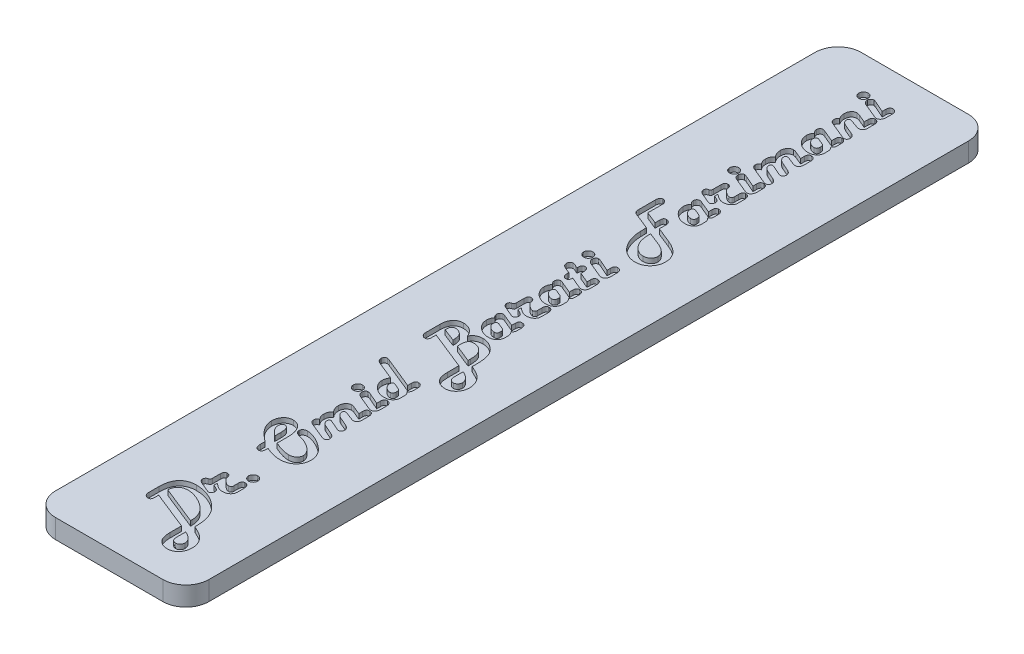
from build123d import *

# Parameters (mm, degrees)
BOSS_EXTRUDE1_DEPTH      = 66.675
BOSS_EXTRUDE1_DEPTH_BACK = 66.675
SKETCH3_W                = 25.4
SKETCH3_H                = 3.175
SKETCH5_OUTSIDE_W        = 54.556
SKETCH5_OUTSIDE_H        = 162.506
CUT_EXTRUDE2_DEPTH       = 68.947967225
CUT_EXTRUDE1_DEPTH       = 0.79375


with BuildPart() as part:
    # Sketch3 → Boss-Extrude1 (new, two sides: drawn at the far end of the back side and taken through both)
    with BuildSketch(Plane.XY.offset(-BOSS_EXTRUDE1_DEPTH_BACK)):
        Rectangle(SKETCH3_W, SKETCH3_H)
    extrude(amount=BOSS_EXTRUDE1_DEPTH + BOSS_EXTRUDE1_DEPTH_BACK)

    # Sketch5 outside → Cut-Extrude2 (cut, through all)
    with BuildSketch(Plane(origin=(0, 1.5875, 0), x_dir=(1, 0, 0), z_dir=(0, 1, 0))):
        Rectangle(SKETCH5_OUTSIDE_W, SKETCH5_OUTSIDE_H)
        with BuildLine():
            Line((12.7, -62.865), (12.7, 62.865))
            ThreePointArc((12.7, 62.865), (11.584076836, 65.559076836), (8.89, 66.675))
            Line((8.89, 66.675), (-8.89, 66.675))
            ThreePointArc((-8.89, 66.675), (-11.584076836, 65.559076836), (-12.7, 62.865))
            Line((-12.7, 62.865), (-12.7, -62.865))
            ThreePointArc((-12.7, -62.865), (-11.584076836, -65.559076836), (-8.89, -66.675))
            Line((-8.89, -66.675), (8.89, -66.675))
            ThreePointArc((8.89, -66.675), (11.584076836, -65.559076836), (12.7, -62.865))
        make_face(mode=Mode.SUBTRACT)
    extrude(amount=-CUT_EXTRUDE2_DEPTH, mode=Mode.SUBTRACT)

    # Sketch4 → Cut-Extrude1 (cut)
    # profile 1 of 25: a face of its own
    with BuildSketch(Plane(origin=(0, 1.5875, 0), x_dir=(1, 0, 0), z_dir=(0, 1, 0))):
        with BuildLine():
            Line((-3.545643193, -54.932438639), (-3.545643193, -55.461762812))
            Line((-3.545643193, -55.461762812), (-3.545643193, -55.605979878))
            add(Edge.make_bspline(
                [(-3.545643193, -55.605979878), (-3.547095122, -55.655725712), (-3.549814938, -55.748911795), (-3.571370094, -55.879384436), (-3.608826542, -55.991008762), (-3.662912082, -56.083274108), (-3.732855113, -56.156479272), (-3.820481404, -56.206238281), (-3.922353573, -56.237211307), (-3.995487767, -56.240017321), (-4.033762491, -56.241485847)],
                knots=[0, 0, 0, 0, 1.305737749, 2.445965353, 3.459324035, 4.379959175, 5.233349143, 6.085046436, 6.997810513, 8, 8, 8, 8], degree=3))
            add(Edge.make_bspline(
                [(-4.033762491, -56.241485847), (-4.083785842, -56.238512315), (-4.18250788, -56.232643994), (-4.32412961, -56.183385328), (-4.449814879, -56.099172071), (-4.560360012, -55.988293583), (-4.649813495, -55.853780587), (-4.715652297, -55.702019557), (-4.756357971, -55.535721453), (-4.760599554, -55.419736038), (-4.762771832, -55.360335426)],
                knots=[0, 0, 0, 0, 0.941902933, 1.858863449, 2.78744378, 3.773831386, 4.79357467, 5.815409039, 6.881186575, 8, 8, 8, 8], degree=3))
            Line((-4.762771832, -55.360335426), (-4.762771832, -55.216118361))
            Line((-4.762771832, -55.216118361), (-4.762771832, -53.648748278))
            add(Edge.make_bspline(
                [(-4.762771832, -53.648748278), (-4.760892536, -53.519767874), (-4.757242081, -53.269228869), (-4.721905802, -52.90530805), (-4.663978736, -52.564462235), (-4.581880253, -52.246795112), (-4.476941321, -51.951889274), (-4.35108176, -51.678630855), (-4.197764362, -51.43054109), (-4.02271335, -51.205430046), (-3.825906259, -51.004818736), (-3.607147739, -50.830812048), (-3.367623492, -50.683978866), (-3.107028426, -50.565175138), (-2.82667889, -50.471159113), (-2.525932194, -50.405619013), (-2.204960839, -50.364985698), (-1.98421096, -50.36083525), (-1.870506512, -50.358697426)],
                knots=[0, 0, 0, 0, 1.240121913, 2.408884614, 3.512215636, 4.562072732, 5.559962685, 6.519078054, 7.449661058, 8.358196616, 9.256317547, 10.145746268, 11.039719344, 11.951275398, 12.894325228, 13.877939151, 14.906963136, 16, 16, 16, 16], degree=3))
            add(Edge.make_bspline(
                [(-1.870506512, -50.358697426), (-1.694362012, -50.362738238), (-1.344435653, -50.370765661), (-0.825373527, -50.442152029), (-0.317171078, -50.553763118), (0.179538721, -50.712047722), (0.665164638, -50.913758103), (1.138047125, -51.163206588), (1.602328555, -51.454221436), (1.894201001, -51.68099211), (2.042371885, -51.79611367)],
                knots=[0, 0, 0, 0, 0.99369571, 1.974062893, 2.951324249, 3.9272385, 4.912259598, 5.915104549, 6.941589699, 8, 8, 8, 8], degree=3))
            add(Edge.make_bspline(
                [(2.042371885, -51.79611367), (2.124030078, -51.863838184), (2.285377964, -51.997654605), (2.509952772, -52.212389437), (2.717606797, -52.432644504), (2.909752662, -52.658748776), (3.083002068, -52.892794027), (3.240966926, -53.132561191), (3.380859519, -53.379464087), (3.505064965, -53.633892561), (3.613396114, -53.8979503), (3.705080829, -54.174175528), (3.784286381, -54.462383773), (3.849706437, -54.763833578), (3.89729731, -55.077900606), (3.934991432, -55.403935755), (3.954667929, -55.743087054), (3.958190969, -55.973633002), (3.959983412, -56.09092957)],
                knots=[0, 0, 0, 0, 1.041972891, 2.058827374, 3.050103684, 4.014970579, 4.971989252, 5.909071109, 6.834104011, 7.757898592, 8.688895906, 9.635856426, 10.615406742, 11.624176682, 12.664286734, 13.734882699, 14.847559518, 16, 16, 16, 16], degree=3))
            Line((3.959983412, -56.09092957), (3.959983412, -56.468112663))
            Line((3.959983412, -56.468112663), (4.112124492, -56.533089583))
            add(Edge.make_bspline(
                [(4.112124492, -56.533089583), (4.180256086, -56.563759398), (4.311336134, -56.622765808), (4.500830041, -56.707474121), (4.67275276, -56.79060682), (4.830141077, -56.86619853), (4.971340894, -56.937303493), (5.096061113, -57.004257834), (5.206537562, -57.063636251), (5.331434643, -57.140417129), (5.476511474, -57.239746627), (5.645419622, -57.36962092), (5.81024758, -57.517325349), (5.914702309, -57.625410543), (5.967928705, -57.680486893)],
                knots=[0, 0, 0, 0, 1.222800361, 2.352575644, 3.396669397, 4.347862466, 5.210067408, 5.983579217, 6.664594993, 7.262130753, 8.381971782, 9.540587582, 10.746771362, 12, 12, 12, 12], degree=3))
            add(Edge.make_bspline(
                [(5.967928705, -57.680486893), (6.034228206, -57.755466386), (6.164747273, -57.903073132), (6.335244326, -58.140425764), (6.477584846, -58.386837982), (6.596901489, -58.640133322), (6.686914711, -58.902936878), (6.752023277, -59.174017624), (6.793160057, -59.453149116), (6.797676702, -59.642332332), (6.799950235, -59.737561077)],
                knots=[0, 0, 0, 0, 1.055914228, 2.078702545, 3.078046045, 4.055880218, 5.029205391, 6.004237832, 6.995397536, 8, 8, 8, 8], degree=3))
            add(Edge.make_bspline(
                [(6.799950235, -59.737561077), (6.797874071, -59.81527228), (6.793795372, -59.96793876), (6.769185135, -60.191445934), (6.724133405, -60.403981011), (6.662332417, -60.606165469), (6.583160855, -60.798488754), (6.486042299, -60.980097766), (6.371342792, -61.150533497), (6.239980779, -61.308540969), (6.09518379, -61.451973909), (5.939924509, -61.577867504), (5.774313724, -61.68349649), (5.600110861, -61.771601727), (5.414390175, -61.837418755), (5.220524879, -61.887485279), (5.016314433, -61.916074578), (4.87714218, -61.919616007), (4.806268168, -61.921419494)],
                knots=[0, 0, 0, 0, 1.126201464, 2.212463691, 3.25287726, 4.269850786, 5.272053028, 6.261782411, 7.249022054, 8.243830034, 9.23438794, 10.19795826, 11.134388982, 12.075812372, 13.02018767, 13.98375799, 14.973220915, 16, 16, 16, 16], degree=3))
            add(Edge.make_bspline(
                [(4.806268168, -61.921419494), (4.718287977, -61.91879699), (4.543984716, -61.913601377), (4.288421744, -61.858995412), (4.039828159, -61.779315956), (3.803954979, -61.663049302), (3.584029627, -61.520021392), (3.388088864, -61.350964), (3.216083992, -61.158715442), (3.124914149, -61.013715629), (3.078832991, -60.940426489)],
                knots=[0, 0, 0, 0, 1.014242392, 2.009381349, 3.004557683, 4.021967388, 5.035219112, 6.025505851, 7.00200576, 8, 8, 8, 8], degree=3))
            add(Edge.make_bspline(
                [(3.078832991, -60.940426489), (3.051469429, -60.889644285), (2.995655247, -60.786062478), (2.928281919, -60.618496945), (2.871671662, -60.438664071), (2.823532763, -60.246171221), (2.788369641, -60.040494155), (2.760901856, -59.822172901), (2.745122068, -59.59093829), (2.743623323, -59.432245967), (2.742854773, -59.350869166)],
                knots=[0, 0, 0, 0, 0.84245226, 1.718372183, 2.633912599, 3.596293803, 4.615457363, 5.681185209, 6.810920853, 8, 8, 8, 8], degree=3))
            Line((2.742854773, -59.350869166), (2.742854773, -57.452275274))
            Line((2.742854773, -57.452275274), (-3.545643193, -54.932438639))
        make_face()
        with BuildLine():
            Line((2.742854773, -55.948297307), (2.742854773, -55.734348914))
            add(Edge.make_bspline(
                [(2.742854773, -55.734348914), (2.741564504, -55.665634102), (2.73900962, -55.529570746), (2.720777645, -55.327487075), (2.693113113, -55.129340129), (2.651335537, -54.935786139), (2.599041168, -54.746852178), (2.535685004, -54.5618304), (2.458782651, -54.381352243), (2.372804564, -54.203583328), (2.271321113, -54.032141143), (2.160982187, -53.863908152), (2.037828763, -53.700619754), (1.905801368, -53.539748109), (1.757738715, -53.386640368), (1.602367504, -53.233590295), (1.431567674, -53.088196266), (1.312133723, -52.995355476), (1.25155523, -52.948265389)],
                knots=[0, 0, 0, 0, 1.003752549, 1.98754731, 2.96218803, 3.924869515, 4.877913061, 5.824875223, 6.779479857, 7.742439712, 8.707376773, 9.687714611, 10.680189018, 11.694008127, 12.725763052, 13.790025714, 14.879071578, 16, 16, 16, 16], degree=3))
            add(Edge.make_bspline(
                [(1.25155523, -52.948265389), (1.131347813, -52.860759777), (0.891548166, -52.686196382), (0.509374144, -52.459262846), (0.113728068, -52.258128422), (-0.293005766, -52.089301185), (-0.698348837, -51.951807287), (-1.0935029, -51.852425987), (-1.473371327, -51.79017675), (-1.722374844, -51.782444247), (-1.843564863, -51.778680838)],
                knots=[0, 0, 0, 0, 1.061151743, 2.116872814, 3.169496409, 4.227969904, 5.258553914, 6.222792805, 7.135033211, 8, 8, 8, 8], degree=3))
            add(Edge.make_bspline(
                [(-1.843564863, -51.778680838), (-1.907546183, -51.77971246), (-2.032690083, -51.781730255), (-2.215572414, -51.802936057), (-2.388228792, -51.83678304), (-2.549706304, -51.886902231), (-2.701391617, -51.948443311), (-2.843078983, -52.024491097), (-2.973283601, -52.115549344), (-3.093039417, -52.218445617), (-3.198539234, -52.334893367), (-3.293638645, -52.459883652), (-3.370569858, -52.597122113), (-3.434532919, -52.743136243), (-3.486209003, -52.898829705), (-3.519074615, -53.06555271), (-3.543273273, -53.24127882), (-3.544839068, -53.361807734), (-3.545643193, -53.423706264)],
                knots=[0, 0, 0, 0, 1.145531499, 2.240595844, 3.292755274, 4.292422607, 5.264114043, 6.220902991, 7.165828125, 8.104908158, 9.042461542, 9.975419986, 10.911970153, 11.852526766, 12.827988561, 13.843075609, 14.892295267, 16, 16, 16, 16], degree=3))
            Line((-3.545643193, -53.423706264), (2.742854773, -55.948297307))
        make_face(mode=Mode.SUBTRACT)
        with BuildLine():
            Line((3.959983412, -57.970505827), (3.959983412, -59.388904436))
            add(Edge.make_bspline(
                [(3.959983412, -59.388904436), (3.962342826, -59.468290849), (3.966757713, -59.616837013), (4.000727162, -59.824715831), (4.058970884, -60.002253851), (4.146616927, -60.147108255), (4.256543008, -60.263235259), (4.394499787, -60.343591775), (4.55583368, -60.392295), (4.671192907, -60.397352416), (4.731782431, -60.400008695)],
                knots=[0, 0, 0, 0, 1.31364871, 2.458071474, 3.475829816, 4.38621616, 5.23967168, 6.094559773, 6.99921559, 8, 8, 8, 8], degree=3))
            add(Edge.make_bspline(
                [(4.731782431, -60.400008695), (4.782846729, -60.397484261), (4.882659896, -60.392549857), (5.024860797, -60.34728275), (5.155483977, -60.276741298), (5.26723375, -60.175851423), (5.363359665, -60.058268596), (5.432244359, -59.92325479), (5.473042101, -59.775293675), (5.478562347, -59.672842621), (5.48139421, -59.620285661)],
                knots=[0, 0, 0, 0, 1.015443884, 1.984844108, 2.946375274, 3.953924431, 4.965428653, 5.959234333, 6.953095811, 8, 8, 8, 8], degree=3))
            add(Edge.make_bspline(
                [(5.48139421, -59.620285661), (5.480166652, -59.580067625), (5.477713976, -59.499711484), (5.458073682, -59.380102191), (5.425372008, -59.262229495), (5.383729007, -59.144520223), (5.325403641, -59.029912396), (5.254608814, -58.917467842), (5.174712015, -58.803958118), (5.044589977, -58.657399254), (4.858094199, -58.479311332), (4.595525881, -58.287854276), (4.29431364, -58.113845571), (4.07414428, -58.019450817), (3.959983412, -57.970505827)],
                knots=[0, 0, 0, 0, 0.609246736, 1.21728261, 1.830931323, 2.461525313, 3.105941494, 3.774613737, 4.474427454, 5.206422339, 6.740961797, 8.372497183, 10.119089455, 12, 12, 12, 12], degree=3))
        make_face(mode=Mode.SUBTRACT)
    # profile 2 of 25: a face of its own
    with BuildSketch(Plane(origin=(0, 1.5875, 0), x_dir=(1, 0, 0), z_dir=(0, 1, 0))):
        with BuildLine():
            Line((-0.40139421, -48.924450788), (0.032841789, -49.113042335))
            add(Edge.make_bspline(
                [(0.032841789, -49.113042335), (0.078760205, -49.134306048), (0.166231274, -49.174811794), (0.283819488, -49.247168466), (0.385761084, -49.321208801), (0.468796341, -49.402096738), (0.533883304, -49.488413013), (0.578799843, -49.580514713), (0.60723926, -49.677144686), (0.610990336, -49.743601962), (0.612879655, -49.777074756)],
                knots=[0, 0, 0, 0, 1.297501196, 2.471640463, 3.537215363, 4.524637192, 5.43567625, 6.296618738, 7.14205136, 8, 8, 8, 8], degree=3))
            add(Edge.make_bspline(
                [(0.612879655, -49.777074756), (0.611761943, -49.816885591), (0.609587532, -49.894334098), (0.581108516, -50.004431145), (0.538568721, -50.105761028), (0.476541403, -50.192721916), (0.404440042, -50.266980557), (0.320597586, -50.320767316), (0.227227608, -50.351894405), (0.162492806, -50.35640141), (0.129514766, -50.358697426)],
                knots=[0, 0, 0, 0, 1.131994738, 2.202197021, 3.220602635, 4.248319073, 5.22801886, 6.155513921, 7.060358075, 8, 8, 8, 8], degree=3))
            add(Edge.make_bspline(
                [(0.129514766, -50.358697426), (0.106179514, -50.356630259), (0.051915089, -50.351823211), (-0.038309142, -50.327683176), (-0.148248779, -50.288351766), (-0.227722894, -50.256031359), (-0.271440371, -50.238252405)],
                knots=[0, 0, 0, 0, 0.667539348, 1.552314029, 2.65356594, 4, 4, 4, 4], degree=3))
            Line((-0.271440371, -50.238252405), (-1.707271812, -49.621764071))
            add(Edge.make_bspline(
                [(-1.707271812, -49.621764071), (-1.748446096, -49.603171103), (-1.827068906, -49.567667601), (-1.932826299, -49.501293785), (-2.023581417, -49.430994227), (-2.098044964, -49.353798096), (-2.156279888, -49.271212271), (-2.195962734, -49.18163935), (-2.223314567, -49.087183519), (-2.225815773, -49.02132145), (-2.227087168, -48.987842905)],
                knots=[0, 0, 0, 0, 1.242093141, 2.371792344, 3.427691145, 4.394328043, 5.313892613, 6.192305435, 7.081125362, 8, 8, 8, 8], degree=3))
            add(Edge.make_bspline(
                [(-2.227087168, -48.987842905), (-2.225720852, -48.955557629), (-2.223127082, -48.894268306), (-2.207661488, -48.806365011), (-2.179405162, -48.728436513), (-2.13892172, -48.660298662), (-2.08723593, -48.601524991), (-2.02280609, -48.554645743), (-1.948354435, -48.515011148), (-1.893082509, -48.498731433), (-1.864167301, -48.490214789)],
                knots=[0, 0, 0, 0, 1.15314347, 2.189090296, 3.173792814, 4.095790583, 5.004376053, 5.947550008, 6.926271946, 8, 8, 8, 8], degree=3))
            Line((-1.864167301, -48.490214789), (-1.704102206, -48.445840308))
            add(Edge.make_bspline(
                [(-1.704102206, -48.445840308), (-1.684845254, -48.440705679), (-1.649573718, -48.43130096), (-1.603832882, -48.408736639), (-1.569345468, -48.38230708), (-1.544863416, -48.346648492), (-1.531890203, -48.296525551), (-1.523531625, -48.226898398), (-1.517260875, -48.134254662), (-1.517154328, -48.064439487), (-1.517095462, -48.025867535)],
                knots=[0, 0, 0, 0, 0.926850573, 1.697643703, 2.362895762, 2.92973869, 3.677374781, 4.746381598, 6.202419277, 8, 8, 8, 8], degree=3))
            Line((-1.517095462, -48.025867535), (-1.517095462, -46.773873232))
            add(Edge.make_bspline(
                [(-1.517095462, -46.773873232), (-1.515702056, -46.720952878), (-1.51309606, -46.621979447), (-1.490897645, -46.483436657), (-1.45572989, -46.365275636), (-1.405383171, -46.26663146), (-1.336597151, -46.191094625), (-1.253085283, -46.13723411), (-1.154889049, -46.1045885), (-1.084703322, -46.100753189), (-1.047993799, -46.098747191)],
                knots=[0, 0, 0, 0, 1.361355543, 2.546053047, 3.599677592, 4.524244374, 5.371169927, 6.197098625, 7.057021238, 8, 8, 8, 8], degree=3))
            add(Edge.make_bspline(
                [(-1.047993799, -46.098747191), (-0.996918167, -46.100545701), (-0.89972732, -46.103968052), (-0.76493708, -46.14702932), (-0.648793438, -46.214399432), (-0.557366278, -46.313889554), (-0.484299221, -46.437769008), (-0.435552078, -46.589158495), (-0.405367977, -46.766325566), (-0.402778246, -46.89311799), (-0.40139421, -46.960879976)],
                knots=[0, 0, 0, 0, 0.994284648, 1.892005291, 2.734571892, 3.588753721, 4.500369607, 5.525254763, 6.677415825, 8, 8, 8, 8], degree=3))
            Line((-0.40139421, -46.960879976), (-0.349095714, -47.016348078))
            add(Edge.make_bspline(
                [(-0.349095714, -47.016348078), (-0.285176378, -47.079760841), (-0.16282523, -47.201142331), (0.019831512, -47.365526966), (0.19204532, -47.504276086), (0.350924397, -47.619892205), (0.501002302, -47.707939841), (0.638463394, -47.772209664), (0.765728988, -47.814529945), (0.848218934, -47.820297651), (0.88705056, -47.823012762)],
                knots=[0, 0, 0, 0, 1.435762249, 2.748263184, 3.91660617, 4.961556361, 5.879059361, 6.685751502, 7.381325737, 8, 8, 8, 8], degree=3))
            add(Edge.make_bspline(
                [(0.88705056, -47.823012762), (0.921061715, -47.822340596), (0.98568879, -47.821063365), (1.074975133, -47.796917998), (1.154008017, -47.765958077), (1.215589806, -47.713830081), (1.265275827, -47.650010764), (1.299057202, -47.571494396), (1.320462123, -47.479712771), (1.322031745, -47.414272826), (1.322871361, -47.379267946)],
                knots=[0, 0, 0, 0, 1.140484469, 2.167117703, 3.098941929, 3.971150526, 4.846255631, 5.80154673, 6.824011975, 8, 8, 8, 8], degree=3))
            Line((1.322871361, -47.379267946), (1.322871361, -46.704141904))
            add(Edge.make_bspline(
                [(1.322871361, -46.704141904), (1.32436563, -46.648612998), (1.327154637, -46.544969993), (1.348029178, -46.399459403), (1.387551487, -46.276412423), (1.440588385, -46.173861585), (1.511348593, -46.094110863), (1.597962563, -46.036930988), (1.701330995, -46.002743608), (1.775327838, -45.999186514), (1.814160265, -45.997319804)],
                knots=[0, 0, 0, 0, 1.364190584, 2.546219988, 3.596843527, 4.525897283, 5.362221888, 6.186477391, 7.048290713, 8, 8, 8, 8], degree=3))
            add(Edge.make_bspline(
                [(1.814160265, -45.997319804), (1.868932408, -46.000188734), (1.974255616, -46.005705497), (2.122212641, -46.052860515), (2.250708756, -46.131147019), (2.355653059, -46.24212831), (2.441175687, -46.378540221), (2.497793885, -46.542194997), (2.535546082, -46.727771263), (2.538464933, -46.859765945), (2.54, -46.929183918)],
                knots=[0, 0, 0, 0, 0.982615473, 1.889504555, 2.759142238, 3.658944971, 4.610088785, 5.631441668, 6.75433984, 8, 8, 8, 8], degree=3))
            Line((2.54, -46.929183918), (2.54, -47.978323448))
            add(Edge.make_bspline(
                [(2.54, -47.978323448), (2.538743063, -48.020125548), (2.536281608, -48.10198644), (2.518072169, -48.221894299), (2.490368348, -48.336518567), (2.448574191, -48.444762112), (2.395563619, -48.547028539), (2.332355573, -48.644548803), (2.255464351, -48.734745288), (2.168468565, -48.818720032), (2.072015732, -48.894098227), (1.969049153, -48.961313962), (1.858271574, -49.016942901), (1.741185011, -49.063109978), (1.616245445, -49.097821909), (1.484770355, -49.122712058), (1.346541434, -49.139418474), (1.25213374, -49.140842776), (1.204011143, -49.141568787)],
                knots=[0, 0, 0, 0, 1.009407673, 1.976719137, 2.923785669, 3.852797958, 4.771676065, 5.702527031, 6.65345443, 7.628144937, 8.618662201, 9.606215811, 10.593522047, 11.607757909, 12.641947342, 13.720607507, 14.838121302, 16, 16, 16, 16], degree=3))
            add(Edge.make_bspline(
                [(1.204011143, -49.141568787), (1.141541464, -49.139321129), (1.01634334, -49.134816502), (0.830349738, -49.101737148), (0.646694301, -49.049685201), (0.4630088, -48.972484412), (0.271762343, -48.867127475), (0.064369716, -48.731073522), (-0.163448457, -48.562451167), (-0.319009463, -48.435446396), (-0.40139421, -48.368184965)],
                knots=[0, 0, 0, 0, 0.822710096, 1.64882809, 2.481516469, 3.333299355, 4.267584386, 5.354441073, 6.598918144, 8, 8, 8, 8], degree=3))
            Line((-0.40139421, -48.368184965), (-0.40139421, -48.924450788))
        make_face()
    # profile 3 of 25: a face of its own
    with BuildSketch(Plane(origin=(0, 1.5875, 0), x_dir=(1, 0, 0), z_dir=(0, 1, 0))):
        with BuildLine():
            add(Edge.make_bspline(
                [(1.120016588, -44.726307866), (1.122686775, -44.675812315), (1.127897779, -44.577267734), (1.171288982, -44.435242658), (1.242213155, -44.304612316), (1.340628947, -44.189384432), (1.455856831, -44.09096864), (1.586487174, -44.020044467), (1.728512249, -43.976653264), (1.82705683, -43.97144226), (1.877552382, -43.968772073)],
                knots=[0, 0, 0, 0, 1.018015329, 1.986707578, 2.970091954, 4, 5.029908046, 6.013292422, 6.981984671, 8, 8, 8, 8], degree=3))
            add(Edge.make_bspline(
                [(1.877552382, -43.968772073), (1.928559168, -43.971501919), (2.028614938, -43.976856831), (2.172850993, -44.019716445), (2.305332157, -44.090506986), (2.42078765, -44.189427509), (2.519237787, -44.304601352), (2.590153205, -44.435245472), (2.633546667, -44.577266993), (2.638757359, -44.675812064), (2.641427387, -44.726307866)],
                knots=[0, 0, 0, 0, 1.023458974, 2.007634331, 2.995409192, 4.02013336, 5.044857529, 6.023292197, 6.987108688, 8, 8, 8, 8], degree=3))
            add(Edge.make_bspline(
                [(2.641427387, -44.726307866), (2.638697703, -44.777314908), (2.633343109, -44.877371178), (2.590481178, -45.021603588), (2.519699507, -45.154098712), (2.4207446, -45.269500085), (2.305343227, -45.368454991), (2.172848103, -45.439236663), (2.028615693, -45.482098593), (1.928559423, -45.487453187), (1.877552382, -45.490182871)],
                knots=[0, 0, 0, 0, 1.018333356, 1.997579833, 2.980407786, 4, 5.019592214, 6.002420167, 6.981666644, 8, 8, 8, 8], degree=3))
            add(Edge.make_bspline(
                [(1.877552382, -45.490182871), (1.827056579, -45.487512844), (1.728511508, -45.482302152), (1.586489987, -45.438908689), (1.455845868, -45.367993272), (1.340672024, -45.269543135), (1.241751501, -45.154087642), (1.17096096, -45.021606478), (1.128101346, -44.877370423), (1.122746434, -44.777314653), (1.120016588, -44.726307866)],
                knots=[0, 0, 0, 0, 1.012891312, 1.976707803, 2.955142471, 3.97986664, 5.004590808, 5.992365669, 6.976541026, 8, 8, 8, 8], degree=3))
        make_face()
    # profile 4 of 25: a face of its own
    with BuildSketch(Plane(origin=(0, 1.5875, 0), x_dir=(1, 0, 0), z_dir=(0, 1, 0))):
        with BuildLine():
            Line((-1.212813303, -39.166819241), (-1.212813303, -39.43306613))
            add(Edge.make_bspline(
                [(-1.212813303, -39.43306613), (-1.21426929, -39.494416349), (-1.216991504, -39.609120935), (-1.238309673, -39.76944464), (-1.275276497, -39.905500658), (-1.327918912, -40.018324748), (-1.395702387, -40.108983554), (-1.483732477, -40.170975844), (-1.585421758, -40.209270199), (-1.658319642, -40.213672496), (-1.696178192, -40.21595877)],
                knots=[0, 0, 0, 0, 1.419195962, 2.653426324, 3.733010354, 4.667897623, 5.521241497, 6.318371221, 7.126668378, 8, 8, 8, 8], degree=3))
            add(Edge.make_bspline(
                [(-1.696178192, -40.21595877), (-1.751006528, -40.212735239), (-1.857392447, -40.206480476), (-2.007196479, -40.154208722), (-2.136513047, -40.067033898), (-2.244229217, -39.946612128), (-2.327602799, -39.795103481), (-2.387130778, -39.6163151), (-2.423471125, -39.410742989), (-2.427702455, -39.264711022), (-2.429941941, -39.187421679)],
                knots=[0, 0, 0, 0, 0.92337427, 1.791665163, 2.639677553, 3.52952705, 4.491466319, 5.537308167, 6.69658787, 8, 8, 8, 8], degree=3))
            Line((-2.429941941, -39.187421679), (-2.429941941, -38.439394703))
            Line((-2.429941941, -38.439394703), (-2.629627109, -38.288838426))
            add(Edge.make_bspline(
                [(-2.629627109, -38.288838426), (-2.720493462, -38.219784229), (-2.898285241, -38.084670757), (-3.151081403, -37.874260511), (-3.386409008, -37.663974445), (-3.606514597, -37.454836979), (-3.807157804, -37.244576491), (-3.990650362, -37.034115618), (-4.157365988, -36.824434285), (-4.304829084, -36.612473476), (-4.43693554, -36.401961743), (-4.551993656, -36.19129994), (-4.64657248, -35.979258446), (-4.727421085, -35.768817774), (-4.786721903, -35.55679468), (-4.832656714, -35.345381662), (-4.857682629, -35.133039618), (-4.862036857, -34.991448216), (-4.864199219, -34.921132231)],
                knots=[0, 0, 0, 0, 1.30802669, 2.559323489, 3.768676217, 4.924993305, 6.038505379, 7.098562152, 8.124610483, 9.107291049, 10.056570851, 10.972332677, 11.8558165, 12.716172862, 13.553726262, 14.376707029, 15.193853278, 16, 16, 16, 16], degree=3))
            add(Edge.make_bspline(
                [(-4.864199219, -34.921132231), (-4.862426535, -34.852942935), (-4.858941824, -34.718897558), (-4.839017954, -34.522598513), (-4.802465569, -34.335290433), (-4.749806205, -34.158545657), (-4.685298393, -33.990146684), (-4.603671158, -33.832880871), (-4.508253822, -33.684754733), (-4.399164626, -33.547031968), (-4.278224452, -33.422571708), (-4.147225858, -33.31409008), (-4.008398202, -33.221029906), (-3.861061319, -33.145243208), (-3.705079345, -33.085026781), (-3.540324485, -33.045436854), (-3.367451928, -33.018349905), (-3.249394681, -33.015877716), (-3.189062538, -33.014614325)],
                knots=[0, 0, 0, 0, 1.150118269, 2.260883243, 3.323180519, 4.363394127, 5.367619612, 6.359758966, 7.345759456, 8.335014678, 9.317830416, 10.266874698, 11.198403929, 12.130784805, 13.055687197, 14.010733927, 14.983402628, 16, 16, 16, 16], degree=3))
            add(Edge.make_bspline(
                [(-3.189062538, -33.014614325), (-3.104832113, -33.017510095), (-2.93972515, -33.023186332), (-2.699543572, -33.072276241), (-2.474105123, -33.151556278), (-2.26341885, -33.263504979), (-2.070886668, -33.411021594), (-1.88994205, -33.586245255), (-1.726262851, -33.79538267), (-1.634186299, -33.951671003), (-1.586826791, -34.032057796)],
                knots=[0, 0, 0, 0, 1.009395235, 1.97859838, 2.92646369, 3.86752839, 4.826781332, 5.82594365, 6.881775663, 8, 8, 8, 8], degree=3))
            add(Edge.make_bspline(
                [(-1.586826791, -34.032057796), (-1.55662824, -34.091769938), (-1.494037575, -34.215531596), (-1.419580403, -34.418347961), (-1.354171921, -34.640535275), (-1.302926809, -34.884449387), (-1.261466292, -35.149407174), (-1.234334776, -35.435740276), (-1.216408615, -35.742888768), (-1.214038822, -35.954395949), (-1.212813303, -36.063775133)],
                knots=[0, 0, 0, 0, 0.769448956, 1.594789189, 2.481600085, 3.433081523, 4.46051123, 5.566245002, 6.741403793, 8, 8, 8, 8], degree=3))
            Line((-1.212813303, -36.063775133), (-1.212813303, -37.669180486))
            add(Edge.make_bspline(
                [(-1.212813303, -37.669180486), (-1.087010893, -37.726744577), (-0.842645706, -37.838560081), (-0.478189236, -37.984707696), (-0.128661611, -38.10832864), (0.206852203, -38.211001782), (0.528030255, -38.290260563), (0.834695868, -38.348423496), (1.127127234, -38.38325133), (1.317503472, -38.387971555), (1.410035522, -38.390265812)],
                knots=[0, 0, 0, 0, 1.211445405, 2.353174967, 3.437405929, 4.457477985, 5.424691169, 6.332973357, 7.189744516, 8, 8, 8, 8], degree=3))
            add(Edge.make_bspline(
                [(1.410035522, -38.390265812), (1.459205722, -38.389423887), (1.555120944, -38.387781563), (1.695433778, -38.372900211), (1.828832708, -38.350241222), (1.954027951, -38.314465458), (2.072083929, -38.272119965), (2.182625136, -38.220023169), (2.283836049, -38.155383525), (2.379113544, -38.084944198), (2.465115503, -38.005635531), (2.539408396, -37.91877354), (2.60219392, -37.824926805), (2.65462262, -37.725901969), (2.694237356, -37.619772547), (2.723529683, -37.507850547), (2.738415039, -37.38906707), (2.741359296, -37.307878609), (2.742854773, -37.266640546)],
                knots=[0, 0, 0, 0, 1.202424749, 2.345543342, 3.448210986, 4.507941062, 5.525875972, 6.514263026, 7.489553778, 8.458747024, 9.409764382, 10.344666136, 11.247860876, 12.166909583, 13.078935934, 14.012944157, 14.990714502, 16, 16, 16, 16], degree=3))
            add(Edge.make_bspline(
                [(2.742854773, -37.266640546), (2.740457288, -37.207795811), (2.735608619, -37.088788363), (2.694046648, -36.911390904), (2.625456154, -36.735525117), (2.533874172, -36.558201518), (2.410642632, -36.384938984), (2.266612953, -36.208513511), (2.091303959, -36.03712624), (1.895749651, -35.864309931), (1.679767062, -35.697533077), (1.447872651, -35.540482731), (1.202745158, -35.395126572), (0.943728873, -35.261366847), (0.672594864, -35.13803896), (0.386896985, -35.027594542), (0.089393947, -34.924638712), (-0.116297701, -34.868704765), (-0.220726678, -34.840307283)],
                knots=[0, 0, 0, 0, 0.695010846, 1.405588225, 2.140927651, 2.923070066, 3.758055212, 4.649627007, 5.61231393, 6.65218466, 7.733968257, 8.835615208, 9.96128691, 11.100921686, 12.280380977, 13.480703348, 14.720961327, 16, 16, 16, 16], degree=3))
            Line((-0.220726678, -34.840307283), (-0.545611275, -34.756312728))
            add(Edge.make_bspline(
                [(-0.545611275, -34.756312728), (-0.598371337, -34.74125322), (-0.69848394, -34.712677691), (-0.835052401, -34.651233631), (-0.952107047, -34.581039776), (-1.047830983, -34.497349738), (-1.121812241, -34.402580326), (-1.176319902, -34.297106573), (-1.205923389, -34.179437088), (-1.210478617, -34.09771484), (-1.212813303, -34.05582984)],
                knots=[0, 0, 0, 0, 1.250445841, 2.372730157, 3.406396095, 4.354352236, 5.256122782, 6.134799598, 7.044031207, 8, 8, 8, 8], degree=3))
            add(Edge.make_bspline(
                [(-1.212813303, -34.05582984), (-1.210604586, -34.011156288), (-1.206276762, -33.923621596), (-1.165387074, -33.798881969), (-1.096461919, -33.688525919), (-1.003670605, -33.59359534), (-0.890521067, -33.515061746), (-0.759115366, -33.460501485), (-0.612899385, -33.425712916), (-0.510431106, -33.422173974), (-0.456862312, -33.420323871)],
                knots=[0, 0, 0, 0, 0.967389218, 1.895531301, 2.811843988, 3.768576709, 4.757598997, 5.779755732, 6.839291463, 8, 8, 8, 8], degree=3))
            add(Edge.make_bspline(
                [(-0.456862312, -33.420323871), (-0.366391531, -33.423361083), (-0.180355877, -33.429606521), (0.103981265, -33.472849175), (0.399598106, -33.54316308), (0.706549161, -33.642661432), (1.025060425, -33.770690605), (1.356560482, -33.924487316), (1.699259595, -34.107621117), (1.927805656, -34.244977948), (2.045541491, -34.315737518)],
                knots=[0, 0, 0, 0, 0.807046067, 1.659534055, 2.560354543, 3.515755023, 4.53535331, 5.621298469, 6.774608457, 8, 8, 8, 8], degree=3))
            add(Edge.make_bspline(
                [(2.045541491, -34.315737518), (2.12732368, -34.367912163), (2.287701792, -34.470228707), (2.516613416, -34.631998138), (2.728817097, -34.799161646), (2.927803095, -34.967533146), (3.108432787, -35.142575933), (3.274054211, -35.320792297), (3.425477549, -35.502173423), (3.557976159, -35.690452164), (3.678050536, -35.879809008), (3.779506203, -36.074910863), (3.867280429, -36.273075211), (3.939045339, -36.475836111), (3.99223795, -36.682953108), (4.032525662, -36.892956857), (4.056908258, -37.107583658), (4.05990172, -37.25231539), (4.061410798, -37.325278253)],
                knots=[0, 0, 0, 0, 1.227045475, 2.406284763, 3.543910265, 4.643470051, 5.702101736, 6.723462229, 7.720261343, 8.688194524, 9.633841195, 10.554483101, 11.467086441, 12.373774163, 13.271726755, 14.169505271, 15.077202105, 16, 16, 16, 16], degree=3))
            add(Edge.make_bspline(
                [(4.061410798, -37.325278253), (4.05970951, -37.414703832), (4.056382372, -37.589589674), (4.017662323, -37.845185009), (3.960153403, -38.088693853), (3.877424822, -38.320067917), (3.769727149, -38.538135532), (3.642134032, -38.746081208), (3.485724704, -38.937808514), (3.311187365, -39.11824674), (3.117086877, -39.280482287), (2.907795126, -39.422495747), (2.685885651, -39.543723038), (2.448923131, -39.640391335), (2.199483978, -39.716156779), (1.936725418, -39.772444861), (1.660134516, -39.803595779), (1.471388789, -39.808002674), (1.375169857, -39.810249224)],
                knots=[0, 0, 0, 0, 1.044742485, 2.043158921, 3.015421232, 3.966880159, 4.908848942, 5.854919629, 6.812792487, 7.7955728, 8.786490818, 9.764699265, 10.748624071, 11.737364435, 12.751401624, 13.793218679, 14.87502544, 16, 16, 16, 16], degree=3))
            add(Edge.make_bspline(
                [(1.375169857, -39.810249224), (1.280004409, -39.808469108), (1.086044468, -39.804840993), (0.789667877, -39.772678409), (0.482708353, -39.72230208), (0.164643393, -39.649565873), (-0.164709203, -39.559001826), (-0.50585386, -39.450222301), (-0.85661431, -39.317249805), (-1.09215776, -39.217774694), (-1.212813303, -39.166819241)],
                knots=[0, 0, 0, 0, 0.850453706, 1.733338647, 2.661808821, 3.62984345, 4.648257091, 5.714515583, 6.829276037, 8, 8, 8, 8], degree=3))
        make_face()
        with BuildLine():
            Line((-2.429941941, -36.83398935), (-2.429941941, -35.791189032))
            add(Edge.make_bspline(
                [(-2.429941941, -35.791189032), (-2.430677831, -35.736243925), (-2.432100862, -35.629993389), (-2.439378349, -35.476051626), (-2.454251198, -35.332870302), (-2.472084019, -35.200363669), (-2.497944753, -35.078137504), (-2.528997072, -34.966890534), (-2.565472785, -34.865399864), (-2.608083319, -34.775244974), (-2.655929817, -34.694778575), (-2.7089611, -34.624819656), (-2.769681576, -34.566787915), (-2.833478158, -34.516925644), (-2.905359348, -34.480305144), (-2.981892519, -34.452893831), (-3.064785762, -34.436889102), (-3.121904899, -34.435371494), (-3.151027268, -34.434597737)],
                knots=[0, 0, 0, 0, 1.535960571, 2.970175942, 4.305755099, 5.558702054, 6.705526926, 7.794722329, 8.785043725, 9.716363504, 10.577368943, 11.398450277, 12.160731187, 12.919715576, 13.652835291, 14.404748467, 15.186656079, 16, 16, 16, 16], degree=3))
            add(Edge.make_bspline(
                [(-3.151027268, -34.434597737), (-3.185139629, -34.436614512), (-3.252434048, -34.440593062), (-3.347796509, -34.475901509), (-3.434909136, -34.53148341), (-3.509322823, -34.609399082), (-3.571499513, -34.703160476), (-3.616214265, -34.810680137), (-3.641371114, -34.930552701), (-3.645119263, -35.013988124), (-3.64707058, -35.057425282)],
                knots=[0, 0, 0, 0, 0.920003968, 1.814917814, 2.714724113, 3.694907296, 4.705553796, 5.743216766, 6.825100332, 8, 8, 8, 8], degree=3))
            add(Edge.make_bspline(
                [(-3.64707058, -35.057425282), (-3.642773033, -35.128610186), (-3.633906378, -35.275478148), (-3.568572123, -35.497720379), (-3.466182677, -35.726761572), (-3.321996292, -35.959111421), (-3.146072803, -36.192690371), (-2.935074491, -36.416911768), (-2.696483672, -36.634302221), (-2.520389849, -36.766227792), (-2.429941941, -36.83398935)],
                knots=[0, 0, 0, 0, 0.766929876, 1.582321849, 2.48000381, 3.466751747, 4.524052777, 5.628490565, 6.781910335, 8, 8, 8, 8], degree=3))
        make_face(mode=Mode.SUBTRACT)
    # profile 5 of 25: a face of its own
    with BuildSketch(Plane(origin=(0, 1.5875, 0), x_dir=(1, 0, 0), z_dir=(0, 1, 0))):
        with BuildLine():
            Line((1.322871361, -26.686496285), (1.322871361, -26.049405513))
            add(Edge.make_bspline(
                [(1.322871361, -26.049405513), (1.324092808, -25.999085121), (1.32638457, -25.904670588), (1.350839102, -25.773129646), (1.386887194, -25.659564829), (1.44343114, -25.567134366), (1.515352965, -25.494283151), (1.603208982, -25.442812598), (1.706984431, -25.411592207), (1.781170801, -25.408957225), (1.820499477, -25.407560333)],
                knots=[0, 0, 0, 0, 1.302233387, 2.443338607, 3.456307843, 4.371922057, 5.223711417, 6.082947778, 6.983706517, 8, 8, 8, 8], degree=3))
            add(Edge.make_bspline(
                [(1.820499477, -25.407560333), (1.874129611, -25.410118739), (1.977456249, -25.415047899), (2.123751577, -25.457922193), (2.249133278, -25.533858468), (2.355174757, -25.635469469), (2.440751898, -25.762603806), (2.497437214, -25.914728149), (2.535688984, -26.087140658), (2.538511189, -26.209761016), (2.54, -26.274447527)],
                knots=[0, 0, 0, 0, 1.008838849, 1.943682012, 2.836054192, 3.743822714, 4.690293662, 5.695347907, 6.784215701, 8, 8, 8, 8], degree=3))
            Line((2.54, -26.274447527), (2.54, -27.360037524))
            add(Edge.make_bspline(
                [(2.54, -27.360037524), (2.538118912, -27.415712614), (2.534498661, -27.522862177), (2.499929033, -27.675106795), (2.447204965, -27.812820603), (2.368711514, -27.930096321), (2.273755351, -28.026888813), (2.16212106, -28.096957231), (2.035098481, -28.138105073), (1.946006693, -28.143367099), (1.899739622, -28.14609977)],
                knots=[0, 0, 0, 0, 1.173489931, 2.258441514, 3.279322295, 4.26903132, 5.215254006, 6.121879313, 7.024655981, 8, 8, 8, 8], degree=3))
            add(Edge.make_bspline(
                [(1.899739622, -28.14609977), (1.864243316, -28.144316643), (1.786782453, -28.140425461), (1.662366153, -28.113983403), (1.519906803, -28.074587134), (1.420366603, -28.038548151), (1.367245843, -28.019315537)],
                knots=[0, 0, 0, 0, 0.774670137, 1.690503163, 2.76751073, 4, 4, 4, 4], degree=3))
            Line((1.367245843, -28.019315537), (0.213509321, -27.575570721))
            add(Edge.make_bspline(
                [(0.213509321, -27.575570721), (0.181598555, -27.564489535), (0.121429587, -27.543595537), (0.057916255, -27.53947204), (0.02808738, -27.537535451)],
                knots=[0, 0, 0, 0, 1.060705078, 2, 2, 2, 2], degree=3))
            add(Edge.make_bspline(
                [(0.02808738, -27.537535451), (0.002063334, -27.537992276), (-0.046976295, -27.538853116), (-0.114540065, -27.557146372), (-0.172407718, -27.584058208), (-0.219677773, -27.623409125), (-0.256688101, -27.673383905), (-0.282232623, -27.734783626), (-0.298003101, -27.806152694), (-0.299290218, -27.857575579), (-0.299966824, -27.884607289)],
                knots=[0, 0, 0, 0, 1.137834258, 2.144131219, 3.045979375, 3.918459232, 4.813130763, 5.747454036, 6.815893575, 8, 8, 8, 8], degree=3))
            add(Edge.make_bspline(
                [(-0.299966824, -27.884607289), (-0.29715314, -27.929327172), (-0.291400814, -28.020752996), (-0.244795249, -28.155666245), (-0.174435607, -28.290196793), (-0.075674935, -28.420472637), (0.046564247, -28.543090447), (0.187913365, -28.656240469), (0.349200646, -28.754786067), (0.465943549, -28.808161175), (0.525715495, -28.835489038)],
                knots=[0, 0, 0, 0, 0.807034206, 1.649909652, 2.555772072, 3.545451764, 4.592483469, 5.680085733, 6.812212258, 8, 8, 8, 8], degree=3))
            Line((0.525715495, -28.835489038), (1.88230679, -29.423450919))
            add(Edge.make_bspline(
                [(1.88230679, -29.423450919), (1.934039068, -29.447840577), (2.033652495, -29.494804244), (2.169522399, -29.578095719), (2.282749254, -29.672439481), (2.376931031, -29.773535646), (2.451270695, -29.883148688), (2.501981439, -30.003364941), (2.535539902, -30.130555653), (2.538502919, -30.218806996), (2.54, -30.263396464)],
                knots=[0, 0, 0, 0, 1.208273227, 2.326598472, 3.357226255, 4.313257142, 5.239085742, 6.139179519, 7.059810397, 8, 8, 8, 8], degree=3))
            add(Edge.make_bspline(
                [(2.54, -30.263396464), (2.53866545, -30.297901772), (2.536039925, -30.365785765), (2.509798035, -30.462994916), (2.46773127, -30.552917894), (2.409673762, -30.631403633), (2.342462606, -30.699332983), (2.265226076, -30.747198927), (2.181470898, -30.778259502), (2.122942693, -30.781538896), (2.093085578, -30.78321182)],
                knots=[0, 0, 0, 0, 1.088313199, 2.141092232, 3.156683537, 4.208535652, 5.21198028, 6.156923438, 7.0597875, 8, 8, 8, 8], degree=3))
            add(Edge.make_bspline(
                [(2.093085578, -30.78321182), (2.068170166, -30.782352096), (2.015760014, -30.780543645), (1.935504851, -30.762641993), (1.848147682, -30.739470828), (1.789645139, -30.716254924), (1.758692163, -30.703971675)],
                knots=[0, 0, 0, 0, 0.863824649, 1.817075307, 2.845041399, 4, 4, 4, 4], degree=3))
            Line((1.758692163, -30.703971675), (1.625568718, -30.64691877))
            Line((1.625568718, -30.64691877), (0.254714197, -30.051032874))
            add(Edge.make_bspline(
                [(0.254714197, -30.051032874), (0.226329013, -30.039042091), (0.173313387, -30.016646645), (0.097815444, -29.990967732), (0.031380934, -29.975159761), (-0.009880487, -29.972857579), (-0.028965525, -29.971792728)],
                knots=[0, 0, 0, 0, 1.247216224, 2.32945297, 3.227305984, 4, 4, 4, 4], degree=3))
            add(Edge.make_bspline(
                [(-0.028965525, -29.971792728), (-0.046623379, -29.972866366), (-0.082137719, -29.97502572), (-0.132478482, -29.997710726), (-0.179169727, -30.03190444), (-0.235413931, -30.093157349), (-0.288871239, -30.191693279), (-0.29621552, -30.280065246), (-0.299966824, -30.325203778)],
                knots=[0, 0, 0, 0, 0.646098691, 1.299465312, 1.995389185, 2.765525403, 4.347898796, 6, 6, 6, 6], degree=3))
            add(Edge.make_bspline(
                [(-0.299966824, -30.325203778), (-0.297358093, -30.371905869), (-0.292214343, -30.463990472), (-0.256126385, -30.59864661), (-0.195255896, -30.724835752), (-0.108674487, -30.842221216), (0.000780351, -30.951872829), (0.133147721, -31.05569744), (0.291597213, -31.148125397), (0.406920606, -31.202015212), (0.467077787, -31.230126242)],
                knots=[0, 0, 0, 0, 0.888822976, 1.752532061, 2.634326399, 3.541737762, 4.516194379, 5.576620865, 6.735870875, 8, 8, 8, 8], degree=3))
            Line((0.467077787, -31.230126242), (1.875967579, -31.848199379))
            add(Edge.make_bspline(
                [(1.875967579, -31.848199379), (1.928221485, -31.873138147), (2.028247535, -31.920876711), (2.164990554, -32.004822834), (2.279371742, -32.098813946), (2.375562895, -32.19929228), (2.449089134, -32.309967395), (2.502704832, -32.428562732), (2.533093553, -32.556164955), (2.537669852, -32.643616559), (2.54, -32.688144924)],
                knots=[0, 0, 0, 0, 1.219730969, 2.33484689, 3.371103352, 4.331965543, 5.255137239, 6.157124354, 7.061649673, 8, 8, 8, 8], degree=3))
            add(Edge.make_bspline(
                [(2.54, -32.688144924), (2.538883622, -32.723230876), (2.536699181, -32.791884313), (2.507404722, -32.890208539), (2.464958975, -32.982071458), (2.404827139, -33.063505548), (2.333362092, -33.131719536), (2.250969041, -33.180747045), (2.161413125, -33.212634158), (2.098105957, -33.215847016), (2.066143928, -33.217469098)],
                knots=[0, 0, 0, 0, 1.063914662, 2.081784754, 3.095585383, 4.130821801, 5.142964538, 6.080223552, 7.030758269, 8, 8, 8, 8], degree=3))
            add(Edge.make_bspline(
                [(2.066143928, -33.217469098), (2.010194439, -33.212834767), (1.888344374, -33.202741851), (1.773344071, -33.160873014), (1.711148075, -33.138228952)],
                knots=[0, 0, 0, 0, 0.918333358, 2, 2, 2, 2], degree=3))
            Line((1.711148075, -33.138228952), (1.571685419, -33.079591244))
            Line((1.571685419, -33.079591244), (-0.981432077, -32.019358094))
            add(Edge.make_bspline(
                [(-0.981432077, -32.019358094), (-1.023598066, -32.000127719), (-1.104617597, -31.963177657), (-1.214342684, -31.896535702), (-1.308259002, -31.823723596), (-1.383402776, -31.741723605), (-1.44358365, -31.653421547), (-1.486644992, -31.557542031), (-1.51312394, -31.454470507), (-1.515757137, -31.383481775), (-1.517095462, -31.347401658)],
                knots=[0, 0, 0, 0, 1.213221707, 2.331135963, 3.355627831, 4.315449995, 5.232827872, 6.143395129, 7.056378105, 8, 8, 8, 8], degree=3))
            add(Edge.make_bspline(
                [(-1.517095462, -31.347401658), (-1.516202355, -31.310299577), (-1.514502326, -31.239675728), (-1.492836949, -31.139345081), (-1.460012287, -31.049725231), (-1.413604611, -30.970016308), (-1.352058747, -30.902785584), (-1.277579884, -30.846249534), (-1.189358503, -30.801658589), (-1.124434127, -30.78220243), (-1.090783478, -30.7721182)],
                knots=[0, 0, 0, 0, 1.138276205, 2.166709906, 3.137669574, 4.062044646, 4.981559819, 5.919942444, 6.921895113, 8, 8, 8, 8], degree=3))
            add(Edge.make_bspline(
                [(-1.090783478, -30.7721182), (-1.131088858, -30.714456199), (-1.206181693, -30.607026296), (-1.301600777, -30.449639422), (-1.379172299, -30.311970313), (-1.43478049, -30.18404286), (-1.472262747, -30.057769488), (-1.499172473, -29.924188897), (-1.515023159, -29.777244463), (-1.51638476, -29.67494671), (-1.517095462, -29.621551284)],
                knots=[0, 0, 0, 0, 1.346925548, 2.509453026, 3.523575207, 4.371109248, 5.174437451, 6.041491896, 6.977735358, 8, 8, 8, 8], degree=3))
            add(Edge.make_bspline(
                [(-1.517095462, -29.621551284), (-1.515735235, -29.563881618), (-1.513075607, -29.451121118), (-1.487689403, -29.287647171), (-1.444154711, -29.13527338), (-1.386073682, -28.993797544), (-1.310723557, -28.863431425), (-1.217686122, -28.745294649), (-1.107823603, -28.638128194), (-1.023995202, -28.577724398), (-0.981432077, -28.547054907)],
                knots=[0, 0, 0, 0, 1.102801135, 2.156288014, 3.154460606, 4.128602279, 5.075087991, 6.025343504, 6.997385731, 8, 8, 8, 8], degree=3))
            add(Edge.make_bspline(
                [(-0.981432077, -28.547054907), (-1.024016311, -28.497546895), (-1.107909007, -28.400014069), (-1.217292486, -28.244151654), (-1.310570063, -28.083321112), (-1.38395086, -27.916903378), (-1.444045523, -27.747091545), (-1.486686621, -27.572524115), (-1.512981807, -27.392539327), (-1.515716402, -27.270849551), (-1.517095462, -27.209481247)],
                knots=[0, 0, 0, 0, 1.062056674, 2.092295418, 3.093435761, 4.08228624, 5.047351069, 6.020953088, 7.001964205, 8, 8, 8, 8], degree=3))
            add(Edge.make_bspline(
                [(-1.517095462, -27.209481247), (-1.51393378, -27.127852664), (-1.507806641, -26.969661656), (-1.455141831, -26.742628456), (-1.364135176, -26.537880881), (-1.243415655, -26.356330902), (-1.096586153, -26.20511933), (-0.927318674, -26.096282464), (-0.742092716, -26.026437042), (-0.611729242, -26.019594874), (-0.545611275, -26.016124652)],
                knots=[0, 0, 0, 0, 1.144086019, 2.217166006, 3.245697009, 4.271260664, 5.261603959, 6.178351064, 7.07609303, 8, 8, 8, 8], degree=3))
            add(Edge.make_bspline(
                [(-0.545611275, -26.016124652), (-0.502186821, -26.017115793), (-0.413718742, -26.01913503), (-0.281336052, -26.043425044), (-0.145954997, -26.077309479), (-0.05820368, -26.112268628), (-0.013117496, -26.130230462)],
                knots=[0, 0, 0, 0, 0.949515968, 1.934436571, 2.938723933, 4, 4, 4, 4], degree=3))
            Line((-0.013117496, -26.130230462), (1.322871361, -26.686496285))
        make_face()
    # profile 6 of 25: a face of its own
    with BuildSketch(Plane(origin=(0, 1.5875, 0), x_dir=(1, 0, 0), z_dir=(0, 1, 0))):
        with BuildLine():
            Line((1.322871361, -23.721330031), (1.322871361, -23.117520121))
            add(Edge.make_bspline(
                [(1.322871361, -23.117520121), (1.324165314, -23.066687691), (1.326607829, -22.97073445), (1.350322936, -22.837437757), (1.387267539, -22.72257665), (1.443440139, -22.629151952), (1.514774193, -22.554307934), (1.603558376, -22.503482737), (1.706637934, -22.469632019), (1.781105109, -22.46736527), (1.820499477, -22.466166123)],
                knots=[0, 0, 0, 0, 1.305122279, 2.463598793, 3.468268802, 4.38797846, 5.242443187, 6.094639849, 6.99203298, 8, 8, 8, 8], degree=3))
            add(Edge.make_bspline(
                [(1.820499477, -22.466166123), (1.874190643, -22.468538175), (1.977789597, -22.473115132), (2.123405754, -22.518598023), (2.249702451, -22.593869016), (2.355160104, -22.69747671), (2.440750028, -22.826015678), (2.497941442, -22.980665622), (2.535461146, -23.156397758), (2.538437486, -23.281592176), (2.54, -23.347316543)],
                knots=[0, 0, 0, 0, 0.999294106, 1.928172372, 2.812101714, 3.718114382, 4.663830439, 5.668552371, 6.776040317, 8, 8, 8, 8], degree=3))
            Line((2.54, -23.347316543), (2.54, -24.198355709))
            add(Edge.make_bspline(
                [(2.54, -24.198355709), (2.537541516, -24.272451103), (2.532875113, -24.413090186), (2.498794095, -24.612586296), (2.439042876, -24.787663532), (2.355218811, -24.936125309), (2.251664663, -25.057238092), (2.126747126, -25.143591742), (1.98327324, -25.19496855), (1.882200522, -25.201389757), (1.830008294, -25.20470556)],
                knots=[0, 0, 0, 0, 1.28711117, 2.443041656, 3.502572821, 4.485077292, 5.389118816, 6.247116561, 7.09484088, 8, 8, 8, 8], degree=3))
            add(Edge.make_bspline(
                [(1.830008294, -25.20470556), (1.798768864, -25.20270898), (1.731521609, -25.198411063), (1.624991705, -25.177087694), (1.507524565, -25.139146461), (1.426239589, -25.107433078), (1.383093872, -25.09059975)],
                knots=[0, 0, 0, 0, 0.809405691, 1.742359281, 2.801653991, 4, 4, 4, 4], degree=3))
            Line((1.383093872, -25.09059975), (-0.769068486, -24.1936013))
            Line((-0.769068486, -24.1936013), (-0.91803996, -24.134963592))
            add(Edge.make_bspline(
                [(-0.91803996, -24.134963592), (-0.965612489, -24.113336542), (-1.056447818, -24.072041697), (-1.179427643, -23.994840585), (-1.282784368, -23.907697667), (-1.368944362, -23.811021682), (-1.43627852, -23.704747143), (-1.482493318, -23.587424563), (-1.511984492, -23.46182456), (-1.515370024, -23.374426295), (-1.517095462, -23.329883711)],
                knots=[0, 0, 0, 0, 1.169966962, 2.233943366, 3.241792019, 4.189384164, 5.125372702, 6.044138547, 7.003193917, 8, 8, 8, 8], degree=3))
            add(Edge.make_bspline(
                [(-1.517095462, -23.329883711), (-1.515327755, -23.292705606), (-1.511893922, -23.220485856), (-1.483224865, -23.11658036), (-1.439440181, -23.019930455), (-1.374995868, -22.93545599), (-1.30082042, -22.862447838), (-1.215659888, -22.808688563), (-1.12195366, -22.777208373), (-1.057206229, -22.77272981), (-1.024221756, -22.770448282)],
                knots=[0, 0, 0, 0, 1.078211172, 2.094462323, 3.11059759, 4.141917063, 5.162215888, 6.120373975, 7.04245663, 8, 8, 8, 8], degree=3))
            add(Edge.make_bspline(
                [(-1.024221756, -22.770448282), (-0.992913878, -22.772737922), (-0.921400871, -22.777967883), (-0.805151648, -22.809836756), (-0.665960727, -22.855375532), (-0.568509353, -22.897882569), (-0.51550002, -22.921004559)],
                knots=[0, 0, 0, 0, 0.704844091, 1.609994759, 2.699940496, 4, 4, 4, 4], degree=3))
            Line((-0.51550002, -22.921004559), (1.322871361, -23.721330031))
        make_face()
    # profile 7 of 25: a face of its own
    with BuildSketch(Plane(origin=(0, 1.5875, 0), x_dir=(1, 0, 0), z_dir=(0, 1, 0))):
        with BuildLine():
            add(Edge.make_bspline(
                [(-3.241361034, -23.024016749), (-3.238598462, -22.9730309), (-3.233179354, -22.873016202), (-3.190919801, -22.728931488), (-3.118870321, -22.598240814), (-3.02297512, -22.481697264), (-2.90643157, -22.385802063), (-2.775740895, -22.313752583), (-2.631656181, -22.271493029), (-2.531641483, -22.266073922), (-2.480655635, -22.26331135)],
                knots=[0, 0, 0, 0, 1.022434278, 2.00562427, 2.98307932, 4, 5.01692068, 5.99437573, 6.977565722, 8, 8, 8, 8], degree=3))
            add(Edge.make_bspline(
                [(-2.480655635, -22.26331135), (-2.429669786, -22.266073922), (-2.329655088, -22.271493029), (-2.185570374, -22.313752583), (-2.054879699, -22.385802063), (-1.93833615, -22.481697264), (-1.842440948, -22.598240814), (-1.770391469, -22.728931488), (-1.728131915, -22.873016202), (-1.722712808, -22.9730309), (-1.719950235, -23.024016749)],
                knots=[0, 0, 0, 0, 1.022434278, 2.00562427, 2.98307932, 4, 5.01692068, 5.99437573, 6.977565722, 8, 8, 8, 8], degree=3))
            add(Edge.make_bspline(
                [(-1.719950235, -23.024016749), (-1.722712808, -23.075002597), (-1.728131915, -23.175017295), (-1.770391469, -23.319102009), (-1.842440948, -23.449792684), (-1.93833615, -23.566336234), (-2.054879699, -23.662231435), (-2.185570374, -23.734280915), (-2.329655088, -23.776540468), (-2.429669786, -23.781959576), (-2.480655635, -23.784722148)],
                knots=[0, 0, 0, 0, 1.022434278, 2.00562427, 2.98307932, 4, 5.01692068, 5.99437573, 6.977565722, 8, 8, 8, 8], degree=3))
            add(Edge.make_bspline(
                [(-2.480655635, -23.784722148), (-2.531641483, -23.781959576), (-2.631656181, -23.776540468), (-2.775740895, -23.734280915), (-2.90643157, -23.662231435), (-3.02297512, -23.566336234), (-3.118870321, -23.449792684), (-3.190919801, -23.319102009), (-3.233179354, -23.175017295), (-3.238598462, -23.075002597), (-3.241361034, -23.024016749)],
                knots=[0, 0, 0, 0, 1.022434278, 2.00562427, 2.98307932, 4, 5.01692068, 5.99437573, 6.977565722, 8, 8, 8, 8], degree=3))
        make_face()
    # profile 8 of 25: a face of its own
    with BuildSketch(Plane(origin=(0, 1.5875, 0), x_dir=(1, 0, 0), z_dir=(0, 1, 0))):
        with BuildLine():
            Line((1.322871361, -18.592907798), (1.322871361, -17.982758676))
            add(Edge.make_bspline(
                [(1.322871361, -17.982758676), (1.324085583, -17.928745772), (1.326361204, -17.827518074), (1.350798079, -17.686568699), (1.386516849, -17.565062516), (1.443456592, -17.466246315), (1.514042571, -17.386713873), (1.60268787, -17.331692853), (1.706812265, -17.298971266), (1.781151158, -17.295308269), (1.820499477, -17.293369408)],
                knots=[0, 0, 0, 0, 1.339701588, 2.510787217, 3.543828326, 4.466429057, 5.320648921, 6.157774521, 7.024891641, 8, 8, 8, 8], degree=3))
            add(Edge.make_bspline(
                [(1.820499477, -17.293369408), (1.874119621, -17.296512447), (1.977535547, -17.302574353), (2.124831744, -17.346472468), (2.249814645, -17.428130597), (2.355877465, -17.536144726), (2.440318593, -17.67069236), (2.497995562, -17.830105041), (2.535519244, -18.011128944), (2.538454682, -18.139972778), (2.54, -18.20780069)],
                knots=[0, 0, 0, 0, 0.979849376, 1.889812729, 2.77094707, 3.678910894, 4.637799531, 5.649104908, 6.762406401, 8, 8, 8, 8], degree=3))
            Line((2.54, -18.20780069), (2.54, -18.930470819))
            add(Edge.make_bspline(
                [(2.54, -18.930470819), (2.538570791, -18.964331719), (2.535807843, -19.029791674), (2.520588346, -19.124461584), (2.491742128, -19.211743807), (2.449550049, -19.290905237), (2.398714923, -19.36554282), (2.334641452, -19.431844278), (2.259641249, -19.491430307), (2.202942714, -19.522914052), (2.173910527, -19.539035139)],
                knots=[0, 0, 0, 0, 1.082585093, 2.092855543, 3.053821482, 4.005249062, 4.951269053, 5.930451193, 6.940298374, 8, 8, 8, 8], degree=3))
            add(Edge.make_bspline(
                [(2.173910527, -19.539035139), (2.229675636, -19.595194871), (2.335790495, -19.702060657), (2.450886239, -19.886430662), (2.528052905, -20.076177373), (2.536041268, -20.207647336), (2.54, -20.272798888)],
                knots=[0, 0, 0, 0, 1.122886276, 2.136728896, 3.076633156, 4, 4, 4, 4], degree=3))
            Line((2.54, -20.272798888), (2.54, -20.951094536))
            add(Edge.make_bspline(
                [(2.54, -20.951094536), (2.538897826, -20.999771074), (2.536744504, -21.094870636), (2.516517962, -21.233697592), (2.487554982, -21.365172916), (2.444376197, -21.489368908), (2.386324985, -21.604897408), (2.318915733, -21.714454867), (2.238154877, -21.816157491), (2.144981001, -21.908368472), (2.04267012, -21.992720766), (1.92985243, -22.064454292), (1.809884874, -22.125755747), (1.681983528, -22.177911412), (1.545322677, -22.214131959), (1.401658684, -22.244215937), (1.249213121, -22.258899276), (1.144867087, -22.261818206), (1.091490136, -22.26331135)],
                knots=[0, 0, 0, 0, 1.059569088, 2.070084681, 3.049801034, 3.98866625, 4.925201859, 5.860676639, 6.786120181, 7.746180153, 8.711191757, 9.668697181, 10.651584036, 11.642987279, 12.670329173, 13.726393889, 14.836964288, 16, 16, 16, 16], degree=3))
            add(Edge.make_bspline(
                [(1.091490136, -22.26331135), (1.008976379, -22.261175078), (0.844859051, -22.256926098), (0.602219799, -22.222988719), (0.366094114, -22.166405316), (0.135292642, -22.091707598), (-0.087173737, -21.989297061), (-0.305682723, -21.870113506), (-0.514688748, -21.723346437), (-0.716866118, -21.561345848), (-0.903013899, -21.385322848), (-1.066199461, -21.200034121), (-1.204983963, -21.009970758), (-1.318394672, -20.813318633), (-1.408662337, -20.611987379), (-1.469687271, -20.403912243), (-1.510127947, -20.191429125), (-1.514761134, -20.04741452), (-1.517095462, -19.97485594)],
                knots=[0, 0, 0, 0, 1.037869484, 2.064290546, 3.075077879, 4.090226022, 5.110582536, 6.151851397, 7.217441473, 8.318747218, 9.409432719, 10.43606894, 11.421182977, 12.365101073, 13.2876, 14.189665274, 15.087902813, 16, 16, 16, 16], degree=3))
            add(Edge.make_bspline(
                [(-1.517095462, -19.97485594), (-1.515810755, -19.921982432), (-1.513311155, -19.819108664), (-1.495779271, -19.668420391), (-1.465871052, -19.526294587), (-1.424425425, -19.3920867), (-1.372216226, -19.265855698), (-1.30726084, -19.14806948), (-1.228564399, -19.039302285), (-1.16855174, -18.973247039), (-1.138327566, -18.939979637)],
                knots=[0, 0, 0, 0, 1.121803277, 2.18264559, 3.213697175, 4.199330704, 5.158999854, 6.107276501, 7.046767688, 8, 8, 8, 8], degree=3))
            Line((-1.138327566, -18.939979637), (-4.024253674, -17.762471071))
            add(Edge.make_bspline(
                [(-4.024253674, -17.762471071), (-4.082312623, -17.737054534), (-4.193276359, -17.688477803), (-4.344859218, -17.603171661), (-4.473456347, -17.509817226), (-4.577671354, -17.407421167), (-4.660637187, -17.298489159), (-4.720423397, -17.181250292), (-4.757028913, -17.055184093), (-4.760840121, -16.968198822), (-4.762771832, -16.924110329)],
                knots=[0, 0, 0, 0, 1.277456106, 2.441506528, 3.500399078, 4.472114744, 5.377577036, 6.24939139, 7.112703862, 8, 8, 8, 8], degree=3))
            add(Edge.make_bspline(
                [(-4.762771832, -16.924110329), (-4.760981556, -16.887469223), (-4.75750458, -16.816306863), (-4.729281443, -16.71426219), (-4.684510802, -16.620188376), (-4.621116054, -16.537622889), (-4.546347382, -16.467382958), (-4.45966015, -16.416983236), (-4.365024316, -16.385423606), (-4.298667007, -16.382167761), (-4.265143717, -16.380522929)],
                knots=[0, 0, 0, 0, 1.071512716, 2.08103358, 3.077429279, 4.104694345, 5.112079157, 6.061990656, 7.020930029, 8, 8, 8, 8], degree=3))
            add(Edge.make_bspline(
                [(-4.265143717, -16.380522929), (-4.206500623, -16.384299458), (-4.080136787, -16.392437104), (-3.961206438, -16.436271437), (-3.897469441, -16.459763075)],
                knots=[0, 0, 0, 0, 0.928162608, 2, 2, 2, 2], degree=3))
            Line((-3.897469441, -16.459763075), (-3.756421981, -16.523155191))
            Line((-3.756421981, -16.523155191), (1.322871361, -18.592907798))
        make_face()
        with BuildLine():
            Line((1.322871361, -20.550139398), (1.322871361, -20.347284625))
            add(Edge.make_bspline(
                [(1.322871361, -20.347284625), (1.320603546, -20.292865162), (1.316375239, -20.191400889), (1.265282859, -20.054076583), (1.182434144, -19.942445633), (1.103147844, -19.900849608), (1.062963683, -19.879767765)],
                knots=[0, 0, 0, 0, 1.143165929, 2.131415749, 3.052957589, 4, 4, 4, 4], degree=3))
            Line((1.062963683, -19.879767765), (0.186567671, -19.494660657))
            add(Edge.make_bspline(
                [(0.186567671, -19.494660657), (0.161362782, -19.483706558), (0.114698894, -19.463426331), (0.047998688, -19.440906189), (-0.009412299, -19.427250611), (-0.04476132, -19.424556402), (-0.060661583, -19.423344526)],
                knots=[0, 0, 0, 0, 1.273731735, 2.358164577, 3.261489682, 4, 4, 4, 4], degree=3))
            add(Edge.make_bspline(
                [(-0.060661583, -19.423344526), (-0.083727541, -19.424478564), (-0.129462164, -19.426727107), (-0.193263469, -19.457439595), (-0.253246608, -19.500158705), (-0.304126671, -19.561721567), (-0.348928828, -19.632998735), (-0.378132127, -19.715937339), (-0.398356769, -19.805889072), (-0.400354636, -19.869076138), (-0.40139421, -19.901955006)],
                knots=[0, 0, 0, 0, 0.845414131, 1.676266757, 2.570781394, 3.553665482, 4.605345708, 5.66820858, 6.786671604, 8, 8, 8, 8], degree=3))
            add(Edge.make_bspline(
                [(-0.40139421, -19.901955006), (-0.400097343, -19.936358542), (-0.397484182, -20.005680931), (-0.378575634, -20.108872332), (-0.34377121, -20.20913305), (-0.299925399, -20.308877706), (-0.239892441, -20.404829285), (-0.1701994, -20.501312856), (-0.085269374, -20.594253024), (0.040968254, -20.714485446), (0.212982483, -20.844541269), (0.433968929, -20.961251263), (0.6649146, -21.033772764), (0.822631285, -21.042052216), (0.901313786, -21.046182711)],
                knots=[0, 0, 0, 0, 0.653993533, 1.317782974, 1.984679741, 2.667861076, 3.384331403, 4.131532254, 4.927993484, 5.773290323, 7.444353822, 9.007494626, 10.507083719, 12, 12, 12, 12], degree=3))
            add(Edge.make_bspline(
                [(0.901313786, -21.046182711), (0.934246882, -21.044888293), (0.996853369, -21.042427578), (1.084114996, -21.017876829), (1.159631328, -20.979709424), (1.221640372, -20.924253232), (1.268649072, -20.852013448), (1.298975881, -20.763835588), (1.320389412, -20.662093443), (1.322013528, -20.588833959), (1.322871361, -20.550139398)],
                knots=[0, 0, 0, 0, 1.059153101, 2.013471606, 2.896951977, 3.765204494, 4.66252443, 5.643067418, 6.75510354, 8, 8, 8, 8], degree=3))
        make_face(mode=Mode.SUBTRACT)
    # profile 9 of 25: a face of its own
    with BuildSketch(Plane(origin=(0, 1.5875, 0), x_dir=(1, 0, 0), z_dir=(0, 1, 0))):
        with BuildLine():
            Line((-3.545643193, -9.008019769), (-3.545643193, -9.611829679))
            Line((-3.545643193, -9.611829679), (-3.545643193, -9.756046745))
            add(Edge.make_bspline(
                [(-3.545643193, -9.756046745), (-3.547115275, -9.806313943), (-3.5498746, -9.900536662), (-3.571138235, -10.032146262), (-3.608863173, -10.144203983), (-3.662832352, -10.236638951), (-3.733309083, -10.309471954), (-3.81995884, -10.361417431), (-3.922428328, -10.391907653), (-3.995513449, -10.394795677), (-4.033762491, -10.396307122)],
                knots=[0, 0, 0, 0, 1.313905367, 2.462833448, 3.471827018, 4.388496459, 5.238210391, 6.09329523, 7.002127513, 8, 8, 8, 8], degree=3))
            add(Edge.make_bspline(
                [(-4.033762491, -10.396307122), (-4.083376342, -10.3936194), (-4.18098117, -10.388331871), (-4.319264006, -10.335082901), (-4.446264817, -10.25405489), (-4.557059754, -10.141322783), (-4.648176988, -10.005523864), (-4.715388398, -9.853291169), (-4.756609776, -9.686359175), (-4.760672773, -9.57034071), (-4.762771832, -9.510402293)],
                knots=[0, 0, 0, 0, 0.930770362, 1.83109515, 2.753046898, 3.752210682, 4.784424036, 5.818027447, 6.872731336, 8, 8, 8, 8], degree=3))
            Line((-4.762771832, -9.510402293), (-4.762771832, -9.366185227))
            Line((-4.762771832, -9.366185227), (-4.762771832, -7.195005234))
            add(Edge.make_bspline(
                [(-4.762771832, -7.195005234), (-4.761039087, -7.110447637), (-4.7576766, -6.946358961), (-4.737782391, -6.707379407), (-4.701176402, -6.483369482), (-4.650963867, -6.273901437), (-4.586337401, -6.078733642), (-4.505035197, -5.899879203), (-4.411625969, -5.734211289), (-4.301544025, -5.585744068), (-4.180257525, -5.450602367), (-4.042024618, -5.337712914), (-3.895831753, -5.236537058), (-3.734352107, -5.158400067), (-3.561350687, -5.095622833), (-3.376310309, -5.051835412), (-3.178670496, -5.02647237), (-3.043336121, -5.022634991), (-2.973529341, -5.020655635)],
                knots=[0, 0, 0, 0, 1.268969022, 2.462504312, 3.595010505, 4.671708063, 5.691977326, 6.674756664, 7.615724069, 8.540082979, 9.443399723, 10.332517725, 11.211971114, 12.105354849, 13.015601627, 13.969272161, 14.952530942, 16, 16, 16, 16], degree=3))
            add(Edge.make_bspline(
                [(-2.973529341, -5.020655635), (-2.912183572, -5.021674317), (-2.791245166, -5.02368257), (-2.612277321, -5.045678568), (-2.438437597, -5.078334293), (-2.268679873, -5.124561006), (-2.104121208, -5.185136211), (-1.943870425, -5.257773992), (-1.788734976, -5.344415957), (-1.639368866, -5.443544682), (-1.497558891, -5.553929612), (-1.364991591, -5.673507927), (-1.24315626, -5.801741074), (-1.131403132, -5.938610237), (-1.031186882, -6.084930266), (-0.942712609, -6.241250632), (-0.862738309, -6.405529231), (-0.819419916, -6.520560857), (-0.797594939, -6.5785169)],
                knots=[0, 0, 0, 0, 1.030068084, 2.030699, 3.024537869, 3.999818113, 4.982459674, 5.967382867, 6.952625866, 7.964254993, 8.976117653, 9.968886108, 10.960702115, 11.944785322, 12.93433559, 13.936028518, 14.960115362, 16, 16, 16, 16], degree=3))
            add(Edge.make_bspline(
                [(-0.797594939, -6.5785169), (-0.756789738, -6.503327747), (-0.677129646, -6.356543154), (-0.526405356, -6.161119395), (-0.353841539, -5.995869746), (-0.159296754, -5.861451363), (0.055599073, -5.755270655), (0.292480008, -5.681630331), (0.54986335, -5.636313933), (0.728374255, -5.631634578), (0.820488837, -5.629219954)],
                knots=[0, 0, 0, 0, 1.031362198, 2.013429794, 2.965071348, 3.904327144, 4.856801495, 5.846971263, 6.889001521, 8, 8, 8, 8], degree=3))
            add(Edge.make_bspline(
                [(0.820488837, -5.629219954), (0.88128575, -5.630455113), (1.003172728, -5.632931388), (1.185894152, -5.652602582), (1.367760821, -5.684762752), (1.549404072, -5.726571188), (1.728152257, -5.785032085), (1.907223471, -5.8525736), (2.084036848, -5.936275033), (2.260943067, -6.028469487), (2.432224771, -6.132533435), (2.595900516, -6.245027981), (2.750119135, -6.366102694), (2.896060754, -6.494753138), (3.034251021, -6.630251417), (3.161627691, -6.775991893), (3.28027191, -6.929270298), (3.35303325, -7.036655802), (3.389454362, -7.090408242)],
                knots=[0, 0, 0, 0, 0.948764185, 1.902103166, 2.864526502, 3.83047521, 4.808315118, 5.797491076, 6.815623647, 7.859374656, 8.910007045, 9.941473385, 10.957500475, 11.968160597, 12.976800743, 13.975824254, 14.986787024, 16, 16, 16, 16], degree=3))
            add(Edge.make_bspline(
                [(3.389454362, -7.090408242), (3.435311137, -7.168323413), (3.529893383, -7.329027952), (3.647336629, -7.594248708), (3.741545059, -7.888820677), (3.823577864, -8.209771262), (3.883101554, -8.559758954), (3.93016418, -8.93665131), (3.953926389, -9.342637676), (3.957917765, -9.622370745), (3.959983412, -9.767140365)],
                knots=[0, 0, 0, 0, 0.782515064, 1.613982502, 2.505153024, 3.458273262, 4.480434598, 5.577304398, 6.74618785, 8, 8, 8, 8], degree=3))
            Line((3.959983412, -9.767140365), (3.959983412, -10.553202611))
            Line((3.959983412, -10.553202611), (4.112124492, -10.61817953))
            add(Edge.make_bspline(
                [(4.112124492, -10.61817953), (4.179691178, -10.648928921), (4.310089279, -10.708272694), (4.498951053, -10.792074738), (4.669896964, -10.876141743), (4.827042958, -10.951148853), (4.968428228, -11.02290696), (5.094205066, -11.088864373), (5.205232421, -11.149153953), (5.331542081, -11.225527447), (5.479813255, -11.322030856), (5.647813028, -11.452932411), (5.811890065, -11.599162629), (5.915250439, -11.706246475), (5.967928705, -11.760822432)],
                knots=[0, 0, 0, 0, 1.216494943, 2.347734382, 3.385374868, 4.337800655, 5.201122989, 5.983291354, 6.665189707, 7.270906275, 8.401748184, 9.561865515, 10.757389388, 12, 12, 12, 12], degree=3))
            add(Edge.make_bspline(
                [(5.967928705, -11.760822432), (6.034250736, -11.835788978), (6.164814157, -11.983370235), (6.334722649, -12.220536227), (6.478066606, -12.465841422), (6.596510725, -12.718513557), (6.686706372, -12.979590648), (6.75204497, -13.247980394), (6.793234314, -13.524486214), (6.797697379, -13.71209982), (6.799950235, -13.806802995)],
                knots=[0, 0, 0, 0, 1.060891432, 2.088500808, 3.087714355, 4.07015769, 5.042777628, 6.011518064, 6.996258544, 8, 8, 8, 8], degree=3))
            add(Edge.make_bspline(
                [(6.799950235, -13.806802995), (6.798806478, -13.883496608), (6.796566601, -14.033689449), (6.76786382, -14.253495155), (6.72582564, -14.463616152), (6.666218905, -14.664272339), (6.58561122, -14.853446436), (6.490543402, -15.033773859), (6.377804045, -15.203963051), (6.247890802, -15.361314483), (6.106310681, -15.505850452), (5.95255739, -15.631134358), (5.788649193, -15.736929938), (5.616377746, -15.824612242), (5.433478291, -15.890849569), (5.242241732, -15.941056319), (5.040612172, -15.969366627), (4.903024996, -15.972979912), (4.833209818, -15.974813383)],
                knots=[0, 0, 0, 0, 1.122672197, 2.198583681, 3.241143832, 4.259502727, 5.258300234, 6.24830661, 7.241965323, 8.242649418, 9.233018611, 10.201038072, 11.141129507, 12.085859005, 13.025950441, 13.98499031, 14.977533619, 16, 16, 16, 16], degree=3))
            add(Edge.make_bspline(
                [(4.833209818, -15.974813383), (4.743133346, -15.972138857), (4.564154387, -15.966824662), (4.302140063, -15.912854341), (4.048273908, -15.832999298), (3.809080335, -15.716873277), (3.587254694, -15.573418796), (3.389810453, -15.404357863), (3.216027639, -15.212611456), (3.124832582, -15.067178196), (3.078832991, -14.993820379)],
                knots=[0, 0, 0, 0, 1.026224309, 2.039073623, 3.039585613, 4.055728173, 5.061958661, 6.045023259, 7.013892508, 8, 8, 8, 8], degree=3))
            add(Edge.make_bspline(
                [(3.078832991, -14.993820379), (3.051466658, -14.943038809), (2.995646824, -14.839458297), (2.928317844, -14.671882605), (2.871372684, -14.491601727), (2.824012473, -14.298935213), (2.787850521, -14.092383269), (2.761186987, -13.873414679), (2.745028173, -13.640643186), (2.743593029, -13.481416717), (2.742854773, -13.399508646)],
                knots=[0, 0, 0, 0, 0.840043849, 1.713459683, 2.626382742, 3.593485996, 4.602156813, 5.680117953, 6.806623897, 8, 8, 8, 8], degree=3))
            Line((2.742854773, -13.399508646), (2.742854773, -11.532610812))
            Line((2.742854773, -11.532610812), (-3.545643193, -9.008019769))
        make_face()
        with BuildLine():
            Line((-1.444194528, -8.328139318), (-1.45053374, -8.014348341))
            add(Edge.make_bspline(
                [(-1.45053374, -8.014348341), (-1.45198508, -7.955155353), (-1.454802338, -7.840253353), (-1.469816268, -7.67316984), (-1.498506049, -7.517344639), (-1.538112013, -7.372578594), (-1.587704462, -7.238323548), (-1.653085626, -7.117594852), (-1.724587083, -7.00439405), (-1.783924632, -6.93907616), (-1.813453607, -6.906571103)],
                knots=[0, 0, 0, 0, 1.188980242, 2.307979575, 3.365066503, 4.366267246, 5.319909528, 6.231060351, 7.119697794, 8, 8, 8, 8], degree=3))
            add(Edge.make_bspline(
                [(-1.813453607, -6.906571103), (-1.847265137, -6.874300092), (-1.916243732, -6.808464295), (-2.032135989, -6.718479076), (-2.165454508, -6.642517839), (-2.306308584, -6.572155234), (-2.451246776, -6.513663946), (-2.594720333, -6.472664972), (-2.73264625, -6.445212452), (-2.823382727, -6.442131749), (-2.867347546, -6.440639046)],
                knots=[0, 0, 0, 0, 0.951495485, 1.941137306, 2.977883418, 4.069850704, 5.146452431, 6.154109755, 7.10560524, 8, 8, 8, 8], degree=3))
            add(Edge.make_bspline(
                [(-2.867347546, -6.440639046), (-2.904404356, -6.441894084), (-2.976303477, -6.444329159), (-3.079023715, -6.461867394), (-3.172668127, -6.489409188), (-3.254714829, -6.532347625), (-3.329055235, -6.583974928), (-3.390957341, -6.650790551), (-3.444378086, -6.727476759), (-3.470463542, -6.785108463), (-3.48383588, -6.814652534)],
                knots=[0, 0, 0, 0, 1.15241049, 2.235953429, 3.234105522, 4.174996894, 5.105494548, 6.03555661, 6.992956108, 8, 8, 8, 8], degree=3))
            add(Edge.make_bspline(
                [(-3.48383588, -6.814652534), (-3.493720367, -6.845618988), (-3.517424209, -6.919879178), (-3.531551726, -7.055311812), (-3.545666596, -7.229016601), (-3.545651523, -7.358176761), (-3.545643193, -7.429556065)],
                knots=[0, 0, 0, 0, 0.627252071, 1.504203836, 2.620718691, 4, 4, 4, 4], degree=3))
            Line((-3.545643193, -7.429556065), (-3.545643193, -7.510381014))
            Line((-3.545643193, -7.510381014), (-1.444194528, -8.328139318))
        make_face(mode=Mode.SUBTRACT)
        with BuildLine():
            Line((2.742854773, -10.028632846), (2.742854773, -9.59598165))
            add(Edge.make_bspline(
                [(2.742854773, -9.59598165), (2.741786616, -9.505074827), (2.739716111, -9.32886202), (2.719547328, -9.072969193), (2.69144994, -8.83332246), (2.646048464, -8.611318994), (2.591998919, -8.404962927), (2.521434116, -8.216842705), (2.442273197, -8.043496152), (2.375853132, -7.939721655), (2.343484439, -7.889148911)],
                knots=[0, 0, 0, 0, 1.226752052, 2.377922951, 3.463095917, 4.481114353, 5.434183921, 6.338839799, 7.190461708, 8, 8, 8, 8], degree=3))
            add(Edge.make_bspline(
                [(2.343484439, -7.889148911), (2.299106021, -7.82865259), (2.209809678, -7.706924495), (2.045188668, -7.546747247), (1.858531428, -7.403090674), (1.650899818, -7.280246508), (1.432728619, -7.177448712), (1.209088918, -7.10456366), (0.985204149, -7.057051406), (0.834983721, -7.051810242), (0.760266326, -7.049203366)],
                knots=[0, 0, 0, 0, 0.967572514, 1.946907805, 2.953987281, 4.003525723, 5.056606173, 6.061997217, 7.036066394, 8, 8, 8, 8], degree=3))
            add(Edge.make_bspline(
                [(0.760266326, -7.049203366), (0.717963466, -7.050049489), (0.636269805, -7.051683488), (0.518452759, -7.066040369), (0.410121442, -7.089613607), (0.311254203, -7.122143215), (0.223269873, -7.166381546), (0.142518701, -7.215914491), (0.073968889, -7.279240843), (0.014442641, -7.351858987), (-0.037449314, -7.43578934), (-0.078650688, -7.533765089), (-0.118171465, -7.64377787), (-0.146395264, -7.769001931), (-0.171055717, -7.907442945), (-0.185118955, -8.06011331), (-0.197556181, -8.226511702), (-0.198203046, -8.34237324), (-0.198539437, -8.402625055)],
                knots=[0, 0, 0, 0, 1.056180458, 2.039655154, 2.958345355, 3.821956831, 4.630289491, 5.413468325, 6.179343411, 6.947940811, 7.753469373, 8.633551087, 9.597361454, 10.669326814, 11.834051265, 13.107430408, 14.495768538, 16, 16, 16, 16], degree=3))
            Line((-0.198539437, -8.402625055), (-0.198539437, -8.846369871))
            Line((-0.198539437, -8.846369871), (2.742854773, -10.028632846))
        make_face(mode=Mode.SUBTRACT)
        with BuildLine():
            Line((3.959983412, -12.050841365), (3.959983412, -13.442298325))
            add(Edge.make_bspline(
                [(3.959983412, -13.442298325), (3.962131469, -13.521719099), (3.966153325, -13.670420406), (4.002737516, -13.877967816), (4.060538549, -14.055574462), (4.148124365, -14.201114433), (4.259704134, -14.316103667), (4.397992598, -14.397441175), (4.56067585, -14.445587706), (4.677026971, -14.450711918), (4.738121643, -14.453402585)],
                knots=[0, 0, 0, 0, 1.309604641, 2.452002308, 3.466627479, 4.374211198, 5.231136963, 6.083393283, 6.993611261, 8, 8, 8, 8], degree=3))
            add(Edge.make_bspline(
                [(4.738121643, -14.453402585), (4.788063481, -14.450649234), (4.886028448, -14.445248314), (5.026927685, -14.402835228), (5.155080758, -14.33092532), (5.267910808, -14.232646487), (5.362270479, -14.115236268), (5.432703318, -13.982801768), (5.472805394, -13.837093147), (5.478491453, -13.736252663), (5.48139421, -13.684773171)],
                knots=[0, 0, 0, 0, 1.007069172, 1.975447917, 2.93982508, 3.953142932, 4.977456925, 5.964909691, 6.961077804, 8, 8, 8, 8], degree=3))
            add(Edge.make_bspline(
                [(5.48139421, -13.684773171), (5.48013784, -13.645085403), (5.477610926, -13.565262114), (5.4582118, -13.446675861), (5.425732413, -13.330246514), (5.382907316, -13.21461388), (5.325904884, -13.100979152), (5.254493193, -12.989909852), (5.174704022, -12.877901263), (5.044144745, -12.733323666), (4.858097674, -12.556390959), (4.595446921, -12.366547712), (4.293891063, -12.1944171), (4.074082542, -12.099902435), (3.959983412, -12.050841365)],
                knots=[0, 0, 0, 0, 0.604489721, 1.215799214, 1.82498573, 2.443877646, 3.091763315, 3.757207903, 4.45426837, 5.18414998, 6.721420115, 8.356974027, 10.108962777, 12, 12, 12, 12], degree=3))
        make_face(mode=Mode.SUBTRACT)
    # profile 10 of 25: a face of its own
    with BuildSketch(Plane(origin=(0, 1.5875, 0), x_dir=(1, 0, 0), z_dir=(0, 1, 0))):
        with BuildLine():
            Line((1.322871361, -1.372439324), (1.322871361, -0.78289264))
            add(Edge.make_bspline(
                [(1.322871361, -0.78289264), (1.324402762, -0.733695548), (1.327285788, -0.64107677), (1.348116821, -0.510719621), (1.387650298, -0.400110627), (1.44161358, -0.308519909), (1.512238507, -0.237197075), (1.59922464, -0.187319738), (1.701697924, -0.156283497), (1.775358445, -0.153570299), (1.814160265, -0.15214108)],
                knots=[0, 0, 0, 0, 1.294659495, 2.437334719, 3.457519937, 4.368220716, 5.213556601, 6.067082152, 6.981805575, 8, 8, 8, 8], degree=3))
            add(Edge.make_bspline(
                [(1.814160265, -0.15214108), (1.868337952, -0.154627664), (1.97223116, -0.159396033), (2.119290838, -0.202919794), (2.245673986, -0.277929666), (2.35232131, -0.379978349), (2.435855725, -0.507225168), (2.49966295, -0.655864986), (2.532482857, -0.827983305), (2.537415282, -0.949179251), (2.54, -1.012689063)],
                knots=[0, 0, 0, 0, 1.020499011, 1.956948009, 2.859423251, 3.7687511, 4.716847855, 5.712717295, 6.801404681, 8, 8, 8, 8], degree=3))
            Line((2.54, -1.012689063), (2.54, -1.697323922))
            add(Edge.make_bspline(
                [(2.54, -1.697323922), (2.538752198, -1.734364274), (2.53636624, -1.805190162), (2.519082612, -1.907275279), (2.488182411, -1.999622804), (2.448396475, -2.085416696), (2.390485676, -2.158045027), (2.325461457, -2.224742485), (2.246510228, -2.280948001), (2.187084669, -2.308916152), (2.156477695, -2.323321073)],
                knots=[0, 0, 0, 0, 1.135251448, 2.170745912, 3.158955961, 4.114801062, 5.050690111, 5.989515837, 6.964505536, 8, 8, 8, 8], degree=3))
            add(Edge.make_bspline(
                [(2.156477695, -2.323321073), (2.214721334, -2.387634154), (2.324649809, -2.509018032), (2.446417298, -2.707118681), (2.52523158, -2.903439686), (2.535185519, -3.035837065), (2.54, -3.099874502)],
                knots=[0, 0, 0, 0, 1.172002926, 2.212026842, 3.135200271, 4, 4, 4, 4], degree=3))
            Line((2.54, -3.099874502), (2.54, -3.708438821))
            add(Edge.make_bspline(
                [(2.54, -3.708438821), (2.538854844, -3.756578386), (2.536618021, -3.850608925), (2.516985654, -3.988112302), (2.485615349, -4.118305588), (2.441176123, -4.242029243), (2.381898565, -4.357231674), (2.31182595, -4.466958976), (2.227302173, -4.567587692), (2.132385541, -4.661789389), (2.025702561, -4.744877327), (1.912093723, -4.820303368), (1.788809417, -4.881893871), (1.658321366, -4.932898218), (1.520263814, -4.972044914), (1.374655749, -5.001384784), (1.22069673, -5.016287914), (1.115288327, -5.0191777), (1.06137888, -5.020655635)],
                knots=[0, 0, 0, 0, 1.038806976, 2.029091485, 2.99167023, 3.926069813, 4.859424868, 5.783114847, 6.730782711, 7.690452028, 8.664715101, 9.645298791, 10.629655371, 11.633506053, 12.665844953, 13.723757455, 14.835852066, 16, 16, 16, 16], degree=3))
            add(Edge.make_bspline(
                [(1.06137888, -5.020655635), (0.978850484, -5.018600785), (0.815751083, -5.014539821), (0.574352025, -4.979739152), (0.339670978, -4.924835719), (0.111461743, -4.8465335), (-0.10914516, -4.745640653), (-0.324675389, -4.625646088), (-0.531039844, -4.479112261), (-0.7296912, -4.315439868), (-0.912598117, -4.13734155), (-1.07442458, -3.951517893), (-1.210092948, -3.75853793), (-1.321426574, -3.559863514), (-1.410137178, -3.35582704), (-1.472077554, -3.145082182), (-1.509462275, -2.928464108), (-1.51454313, -2.782002283), (-1.517095462, -2.708428182)],
                knots=[0, 0, 0, 0, 1.038436407, 2.05224338, 3.063582843, 4.068804017, 5.083657321, 6.113884954, 7.169134107, 8.264944544, 9.351250422, 10.379092992, 11.362431842, 12.315140492, 13.241586482, 14.156891473, 15.074126981, 16, 16, 16, 16], degree=3))
            add(Edge.make_bspline(
                [(-1.517095462, -2.708428182), (-1.515755685, -2.653455546), (-1.513159227, -2.546919849), (-1.496680424, -2.392225731), (-1.464294609, -2.249204895), (-1.422123756, -2.117286001), (-1.36808566, -1.996617482), (-1.300824882, -1.888123773), (-1.221997094, -1.789794202), (-1.158780857, -1.735508055), (-1.127233945, -1.708417542)],
                knots=[0, 0, 0, 0, 1.187941941, 2.302203992, 3.354530118, 4.350764151, 5.29067738, 6.202947275, 7.103213569, 8, 8, 8, 8], degree=3))
            add(Edge.make_bspline(
                [(-1.127233945, -1.708417542), (-1.158416063, -1.68584595), (-1.218990377, -1.641998426), (-1.298554606, -1.566781678), (-1.366556595, -1.487119233), (-1.42035001, -1.40061636), (-1.463380359, -1.309694474), (-1.496089455, -1.214291347), (-1.513154016, -1.112612873), (-1.515760658, -1.043384818), (-1.517095462, -1.007934654)],
                knots=[0, 0, 0, 0, 1.103205467, 2.143084487, 3.132610165, 4.099600995, 5.055365417, 6.013769083, 6.982894815, 8, 8, 8, 8], degree=3))
            add(Edge.make_bspline(
                [(-1.517095462, -1.007934654), (-1.515207371, -0.970272738), (-1.511513304, -0.896586843), (-1.484596999, -0.791459574), (-1.438693816, -0.6961654), (-1.375437547, -0.612992295), (-1.298958419, -0.54321961), (-1.211165407, -0.493229158), (-1.115187491, -0.460933891), (-1.047729675, -0.457952501), (-1.013128135, -0.45642324)],
                knots=[0, 0, 0, 0, 1.08453349, 2.121900051, 3.102199503, 4.112869643, 5.115253576, 6.062989376, 7.006437589, 8, 8, 8, 8], degree=3))
            add(Edge.make_bspline(
                [(-1.013128135, -0.45642324), (-0.987701446, -0.457350734), (-0.933759726, -0.459318376), (-0.849863633, -0.476481846), (-0.759121979, -0.503407506), (-0.698066289, -0.528727794), (-0.666056297, -0.542002597)],
                knots=[0, 0, 0, 0, 0.847236183, 1.797378234, 2.845219729, 4, 4, 4, 4], degree=3))
            Line((-0.666056297, -0.542002597), (-0.525008838, -0.600640305))
            Line((-0.525008838, -0.600640305), (1.322871361, -1.372439324))
        make_face()
        with BuildLine():
            Line((1.322871361, -3.313822895), (1.322871361, -3.179114647))
            add(Edge.make_bspline(
                [(1.322871361, -3.179114647), (1.322128788, -3.145245169), (1.320692652, -3.079741693), (1.304915601, -2.985796197), (1.277832555, -2.901109909), (1.241132992, -2.824812469), (1.193224679, -2.758024049), (1.135296695, -2.699662917), (1.065703745, -2.651457202), (1.013718517, -2.627359622), (0.986893143, -2.61492481)],
                knots=[0, 0, 0, 0, 1.157664044, 2.238919033, 3.244614913, 4.190073881, 5.122668863, 6.042574887, 6.989931157, 8, 8, 8, 8], degree=3))
            Line((0.986893143, -2.61492481), (0.118421146, -2.253589745))
            add(Edge.make_bspline(
                [(0.118421146, -2.253589745), (0.067407044, -2.231986132), (-0.024165643, -2.193206642), (-0.123047486, -2.184531244), (-0.166843379, -2.180688811)],
                knots=[0, 0, 0, 0, 1.114177243, 2, 2, 2, 2], degree=3))
            add(Edge.make_bspline(
                [(-0.166843379, -2.180688811), (-0.188698981, -2.182820313), (-0.232788773, -2.18712024), (-0.297532987, -2.213481059), (-0.354091437, -2.261921996), (-0.405772459, -2.323583856), (-0.450349979, -2.396826333), (-0.479310385, -2.480742441), (-0.499706329, -2.570633634), (-0.501760849, -2.633289388), (-0.502821597, -2.665638503)],
                knots=[0, 0, 0, 0, 0.809745278, 1.63351721, 2.536886947, 3.535238575, 4.604334403, 5.686212968, 6.805393632, 8, 8, 8, 8], degree=3))
            add(Edge.make_bspline(
                [(-0.502821597, -2.665638503), (-0.501711614, -2.698502799), (-0.499469863, -2.764876389), (-0.47749022, -2.863306049), (-0.444173912, -2.960675546), (-0.396991801, -3.057296953), (-0.336769498, -3.153226028), (-0.263464874, -3.249157757), (-0.175087123, -3.342174964), (-0.045445648, -3.464233653), (0.129292497, -3.59606548), (0.350179754, -3.714294748), (0.576421851, -3.789264474), (0.730147636, -3.798805299), (0.806225611, -3.803526996)],
                knots=[0, 0, 0, 0, 0.627706518, 1.267732443, 1.919531944, 2.592823818, 3.31892668, 4.082778462, 4.897707917, 5.769757387, 7.487317347, 9.064628885, 10.547302323, 12, 12, 12, 12], degree=3))
            add(Edge.make_bspline(
                [(0.806225611, -3.803526996), (0.84646484, -3.80199325), (0.922866116, -3.799081164), (1.030058926, -3.777916996), (1.121546306, -3.739504281), (1.197211217, -3.684982789), (1.253321395, -3.612044589), (1.295899357, -3.52627568), (1.31879445, -3.424323217), (1.321464219, -3.351961981), (1.322871361, -3.313822895)],
                knots=[0, 0, 0, 0, 1.183295301, 2.246694931, 3.193249576, 4.081935609, 4.9554176, 5.872573361, 6.878707581, 8, 8, 8, 8], degree=3))
        make_face(mode=Mode.SUBTRACT)
    # profile 11 of 25: a face of its own
    with BuildSketch(Plane(origin=(0, 1.5875, 0), x_dir=(1, 0, 0), z_dir=(0, 1, 0))):
        with BuildLine():
            Line((-0.40139421, 1.383532945), (0.032841789, 1.194941398))
            add(Edge.make_bspline(
                [(0.032841789, 1.194941398), (0.078760205, 1.173677685), (0.166231274, 1.133171939), (0.283819488, 1.060815267), (0.385761084, 0.986774932), (0.468796341, 0.905886994), (0.533883304, 0.81957072), (0.578799843, 0.727469019), (0.60723926, 0.630839047), (0.610990336, 0.564381771), (0.612879655, 0.530908977)],
                knots=[0, 0, 0, 0, 1.297501196, 2.471640463, 3.537215363, 4.524637192, 5.43567625, 6.296618738, 7.14205136, 8, 8, 8, 8], degree=3))
            add(Edge.make_bspline(
                [(0.612879655, 0.530908977), (0.611761943, 0.491098142), (0.609587532, 0.413649635), (0.581108516, 0.303552588), (0.538568721, 0.202222704), (0.476541403, 0.115261817), (0.404440042, 0.041003176), (0.320597586, -0.012783583), (0.227227608, -0.043910672), (0.162492806, -0.048417677), (0.129514766, -0.050713693)],
                knots=[0, 0, 0, 0, 1.131994738, 2.202197021, 3.220602635, 4.248319073, 5.22801886, 6.155513921, 7.060358075, 8, 8, 8, 8], degree=3))
            add(Edge.make_bspline(
                [(0.129514766, -0.050713693), (0.106179514, -0.048646526), (0.051915089, -0.043839478), (-0.038309142, -0.019699443), (-0.148248779, 0.019631967), (-0.227722894, 0.051952374), (-0.271440371, 0.069731328)],
                knots=[0, 0, 0, 0, 0.667539348, 1.552314029, 2.65356594, 4, 4, 4, 4], degree=3))
            Line((-0.271440371, 0.069731328), (-1.707271812, 0.686219662))
            add(Edge.make_bspline(
                [(-1.707271812, 0.686219662), (-1.748446096, 0.704812629), (-1.827068906, 0.740316132), (-1.932826299, 0.806689948), (-2.023581417, 0.876989506), (-2.098044964, 0.954185637), (-2.156279888, 1.036771462), (-2.195962734, 1.126344383), (-2.223314567, 1.220800214), (-2.225815773, 1.286662283), (-2.227087168, 1.320140828)],
                knots=[0, 0, 0, 0, 1.242093141, 2.371792344, 3.427691145, 4.394328043, 5.313892613, 6.192305435, 7.081125362, 8, 8, 8, 8], degree=3))
            add(Edge.make_bspline(
                [(-2.227087168, 1.320140828), (-2.225720852, 1.352426103), (-2.223127082, 1.413715427), (-2.207661488, 1.501618722), (-2.179405162, 1.57954722), (-2.13892172, 1.647685071), (-2.08723593, 1.706458742), (-2.02280609, 1.753337989), (-1.948354435, 1.792972585), (-1.893082509, 1.809252299), (-1.864167301, 1.817768943)],
                knots=[0, 0, 0, 0, 1.15314347, 2.189090296, 3.173792814, 4.095790583, 5.004376053, 5.947550008, 6.926271946, 8, 8, 8, 8], degree=3))
            Line((-1.864167301, 1.817768943), (-1.704102206, 1.862143425))
            add(Edge.make_bspline(
                [(-1.704102206, 1.862143425), (-1.684845254, 1.867278054), (-1.649573718, 1.876682773), (-1.603832882, 1.899247094), (-1.569345468, 1.925676653), (-1.544863416, 1.961335241), (-1.531890203, 2.011458182), (-1.523531625, 2.081085335), (-1.517260875, 2.173729071), (-1.517154328, 2.243544246), (-1.517095462, 2.282116198)],
                knots=[0, 0, 0, 0, 0.926850573, 1.697643703, 2.362895762, 2.92973869, 3.677374781, 4.746381598, 6.202419277, 8, 8, 8, 8], degree=3))
            Line((-1.517095462, 2.282116198), (-1.517095462, 3.5341105))
            add(Edge.make_bspline(
                [(-1.517095462, 3.5341105), (-1.515702056, 3.587030855), (-1.51309606, 3.686004286), (-1.490897645, 3.824547076), (-1.45572989, 3.942708097), (-1.405383171, 4.041352273), (-1.336597151, 4.116889107), (-1.253085283, 4.170749623), (-1.154889049, 4.203395233), (-1.084703322, 4.207230544), (-1.047993799, 4.209236542)],
                knots=[0, 0, 0, 0, 1.361355543, 2.546053047, 3.599677592, 4.524244374, 5.371169927, 6.197098625, 7.057021238, 8, 8, 8, 8], degree=3))
            add(Edge.make_bspline(
                [(-1.047993799, 4.209236542), (-0.996918167, 4.207438032), (-0.89972732, 4.204015681), (-0.76493708, 4.160954413), (-0.648793438, 4.093584301), (-0.557366278, 3.994094179), (-0.484299221, 3.870214725), (-0.435552078, 3.718825238), (-0.405367977, 3.541658167), (-0.402778246, 3.414865743), (-0.40139421, 3.347103756)],
                knots=[0, 0, 0, 0, 0.994284648, 1.892005291, 2.734571892, 3.588753721, 4.500369607, 5.525254763, 6.677415825, 8, 8, 8, 8], degree=3))
            Line((-0.40139421, 3.347103756), (-0.349095714, 3.291635654))
            add(Edge.make_bspline(
                [(-0.349095714, 3.291635654), (-0.285176378, 3.228222892), (-0.16282523, 3.106841402), (0.019831512, 2.942456767), (0.19204532, 2.803707647), (0.350924397, 2.688091528), (0.501002302, 2.600043892), (0.638463394, 2.535774069), (0.765728988, 2.493453788), (0.848218934, 2.487686082), (0.88705056, 2.484970971)],
                knots=[0, 0, 0, 0, 1.435762249, 2.748263184, 3.91660617, 4.961556361, 5.879059361, 6.685751502, 7.381325737, 8, 8, 8, 8], degree=3))
            add(Edge.make_bspline(
                [(0.88705056, 2.484970971), (0.921061715, 2.485643136), (0.98568879, 2.486920368), (1.074975133, 2.511065735), (1.154008017, 2.542025656), (1.215589806, 2.594153652), (1.265275827, 2.657972968), (1.299057202, 2.736489336), (1.320462123, 2.828270962), (1.322031745, 2.893710907), (1.322871361, 2.928715787)],
                knots=[0, 0, 0, 0, 1.140484469, 2.167117703, 3.098941929, 3.971150526, 4.846255631, 5.80154673, 6.824011975, 8, 8, 8, 8], degree=3))
            Line((1.322871361, 2.928715787), (1.322871361, 3.603841829))
            add(Edge.make_bspline(
                [(1.322871361, 3.603841829), (1.32436563, 3.659370735), (1.327154637, 3.76301374), (1.348029178, 3.90852433), (1.387551487, 4.03157131), (1.440588385, 4.134122148), (1.511348593, 4.21387287), (1.597962563, 4.271052745), (1.701330995, 4.305240125), (1.775327838, 4.308797219), (1.814160265, 4.310663929)],
                knots=[0, 0, 0, 0, 1.364190584, 2.546219988, 3.596843527, 4.525897283, 5.362221888, 6.186477391, 7.048290713, 8, 8, 8, 8], degree=3))
            add(Edge.make_bspline(
                [(1.814160265, 4.310663929), (1.868932408, 4.307794999), (1.974255616, 4.302278236), (2.122212641, 4.255123218), (2.250708756, 4.176836714), (2.355653059, 4.065855423), (2.441175687, 3.929443512), (2.497793885, 3.765788736), (2.535546082, 3.58021247), (2.538464933, 3.448217787), (2.54, 3.378799815)],
                knots=[0, 0, 0, 0, 0.982615473, 1.889504555, 2.759142238, 3.658944971, 4.610088785, 5.631441668, 6.75433984, 8, 8, 8, 8], degree=3))
            Line((2.54, 3.378799815), (2.54, 2.329660285))
            add(Edge.make_bspline(
                [(2.54, 2.329660285), (2.538743063, 2.287858185), (2.536281608, 2.205997293), (2.518072169, 2.086089434), (2.490368348, 1.971465166), (2.448574191, 1.863221621), (2.395563619, 1.760955194), (2.332355573, 1.66343493), (2.255464351, 1.573238444), (2.168468565, 1.489263701), (2.072015732, 1.413885506), (1.969049153, 1.346669771), (1.858271574, 1.291040832), (1.741185011, 1.244873755), (1.616245445, 1.210161824), (1.484770355, 1.185271675), (1.346541434, 1.168565259), (1.25213374, 1.167140957), (1.204011143, 1.166414945)],
                knots=[0, 0, 0, 0, 1.009407673, 1.976719137, 2.923785669, 3.852797958, 4.771676065, 5.702527031, 6.65345443, 7.628144937, 8.618662201, 9.606215811, 10.593522047, 11.607757909, 12.641947342, 13.720607507, 14.838121302, 16, 16, 16, 16], degree=3))
            add(Edge.make_bspline(
                [(1.204011143, 1.166414945), (1.141541464, 1.168662604), (1.01634334, 1.173167231), (0.830349738, 1.206246584), (0.646694301, 1.258298532), (0.4630088, 1.335499321), (0.271762343, 1.440856258), (0.064369716, 1.576910211), (-0.163448457, 1.745532566), (-0.319009463, 1.872537337), (-0.40139421, 1.939798768)],
                knots=[0, 0, 0, 0, 0.822710096, 1.64882809, 2.481516469, 3.333299355, 4.267584386, 5.354441073, 6.598918144, 8, 8, 8, 8], degree=3))
            Line((-0.40139421, 1.939798768), (-0.40139421, 1.383532945))
        make_face()
    # profile 12 of 25: a face of its own
    with BuildSketch(Plane(origin=(0, 1.5875, 0), x_dir=(1, 0, 0), z_dir=(0, 1, 0))):
        with BuildLine():
            Line((1.322871361, 8.161735012), (1.322871361, 8.751281696))
            add(Edge.make_bspline(
                [(1.322871361, 8.751281696), (1.324402762, 8.800478789), (1.327285788, 8.893097567), (1.348116821, 9.023454716), (1.387650298, 9.13406371), (1.44161358, 9.225654427), (1.512238507, 9.296977261), (1.59922464, 9.346854598), (1.701697924, 9.37789084), (1.775358445, 9.380604038), (1.814160265, 9.382033257)],
                knots=[0, 0, 0, 0, 1.294659495, 2.437334719, 3.457519937, 4.368220716, 5.213556601, 6.067082152, 6.981805575, 8, 8, 8, 8], degree=3))
            add(Edge.make_bspline(
                [(1.814160265, 9.382033257), (1.868337952, 9.379546673), (1.97223116, 9.374778304), (2.119290838, 9.331254542), (2.245673986, 9.25624467), (2.35232131, 9.154195987), (2.435855725, 9.026949169), (2.49966295, 8.87830935), (2.532482857, 8.706191031), (2.537415282, 8.584995085), (2.54, 8.521485274)],
                knots=[0, 0, 0, 0, 1.020499011, 1.956948009, 2.859423251, 3.7687511, 4.716847855, 5.712717295, 6.801404681, 8, 8, 8, 8], degree=3))
            Line((2.54, 8.521485274), (2.54, 7.836850415))
            add(Edge.make_bspline(
                [(2.54, 7.836850415), (2.538752198, 7.799810063), (2.53636624, 7.728984174), (2.519082612, 7.626899057), (2.488182411, 7.534551533), (2.448396475, 7.448757641), (2.390485676, 7.37612931), (2.325461457, 7.309431851), (2.246510228, 7.253226335), (2.187084669, 7.225258184), (2.156477695, 7.210853263)],
                knots=[0, 0, 0, 0, 1.135251448, 2.170745912, 3.158955961, 4.114801062, 5.050690111, 5.989515837, 6.964505536, 8, 8, 8, 8], degree=3))
            add(Edge.make_bspline(
                [(2.156477695, 7.210853263), (2.214721334, 7.146540183), (2.324649809, 7.025156305), (2.446417298, 6.827055656), (2.52523158, 6.630734651), (2.535185519, 6.498337271), (2.54, 6.434299835)],
                knots=[0, 0, 0, 0, 1.172002926, 2.212026842, 3.135200271, 4, 4, 4, 4], degree=3))
            Line((2.54, 6.434299835), (2.54, 5.825735515))
            add(Edge.make_bspline(
                [(2.54, 5.825735515), (2.538854844, 5.777595951), (2.536618021, 5.683565411), (2.516985654, 5.546062034), (2.485615349, 5.415868749), (2.441176123, 5.292145093), (2.381898565, 5.176942662), (2.31182595, 5.06721536), (2.227302173, 4.966586645), (2.132385541, 4.872384948), (2.025702561, 4.78929701), (1.912093723, 4.713870968), (1.788809417, 4.652280466), (1.658321366, 4.601276119), (1.520263814, 4.562129422), (1.374655749, 4.532789553), (1.22069673, 4.517886422), (1.115288327, 4.514996637), (1.06137888, 4.513518702)],
                knots=[0, 0, 0, 0, 1.038806976, 2.029091485, 2.99167023, 3.926069813, 4.859424868, 5.783114847, 6.730782711, 7.690452028, 8.664715101, 9.645298791, 10.629655371, 11.633506053, 12.665844953, 13.723757455, 14.835852066, 16, 16, 16, 16], degree=3))
            add(Edge.make_bspline(
                [(1.06137888, 4.513518702), (0.978850484, 4.515573552), (0.815751083, 4.519634515), (0.574352025, 4.554435184), (0.339670978, 4.609338617), (0.111461743, 4.687640836), (-0.10914516, 4.788533684), (-0.324675389, 4.908528248), (-0.531039844, 5.055062076), (-0.7296912, 5.218734468), (-0.912598117, 5.396832786), (-1.07442458, 5.582656444), (-1.210092948, 5.775636407), (-1.321426574, 5.974310822), (-1.410137178, 6.178347297), (-1.472077554, 6.389092154), (-1.509462275, 6.605710228), (-1.51454313, 6.752172054), (-1.517095462, 6.825746155)],
                knots=[0, 0, 0, 0, 1.038436407, 2.05224338, 3.063582843, 4.068804017, 5.083657321, 6.113884954, 7.169134107, 8.264944544, 9.351250422, 10.379092992, 11.362431842, 12.315140492, 13.241586482, 14.156891473, 15.074126981, 16, 16, 16, 16], degree=3))
            add(Edge.make_bspline(
                [(-1.517095462, 6.825746155), (-1.515755685, 6.880718791), (-1.513159227, 6.987254488), (-1.496680424, 7.141948606), (-1.464294609, 7.284969441), (-1.422123756, 7.416888335), (-1.36808566, 7.537556855), (-1.300824882, 7.646050564), (-1.221997094, 7.744380134), (-1.158780857, 7.798666281), (-1.127233945, 7.825756794)],
                knots=[0, 0, 0, 0, 1.187941941, 2.302203992, 3.354530118, 4.350764151, 5.29067738, 6.202947275, 7.103213569, 8, 8, 8, 8], degree=3))
            add(Edge.make_bspline(
                [(-1.127233945, 7.825756794), (-1.158416063, 7.848328386), (-1.218990377, 7.892175911), (-1.298554606, 7.967392659), (-1.366556595, 8.047055103), (-1.42035001, 8.133557976), (-1.463380359, 8.224479863), (-1.496089455, 8.319882989), (-1.513154016, 8.421561464), (-1.515760658, 8.490789518), (-1.517095462, 8.526239683)],
                knots=[0, 0, 0, 0, 1.103205467, 2.143084487, 3.132610165, 4.099600995, 5.055365417, 6.013769083, 6.982894815, 8, 8, 8, 8], degree=3))
            add(Edge.make_bspline(
                [(-1.517095462, 8.526239683), (-1.515207371, 8.563901598), (-1.511513304, 8.637587493), (-1.484596999, 8.742714763), (-1.438693816, 8.838008937), (-1.375437547, 8.921182042), (-1.298958419, 8.990954726), (-1.211165407, 9.040945179), (-1.115187491, 9.073240445), (-1.047729675, 9.076221835), (-1.013128135, 9.077751097)],
                knots=[0, 0, 0, 0, 1.08453349, 2.121900051, 3.102199503, 4.112869643, 5.115253576, 6.062989376, 7.006437589, 8, 8, 8, 8], degree=3))
            add(Edge.make_bspline(
                [(-1.013128135, 9.077751097), (-0.987701446, 9.076823603), (-0.933759726, 9.07485596), (-0.849863633, 9.05769249), (-0.759121979, 9.03076683), (-0.698066289, 9.005446542), (-0.666056297, 8.99217174)],
                knots=[0, 0, 0, 0, 0.847236183, 1.797378234, 2.845219729, 4, 4, 4, 4], degree=3))
            Line((-0.666056297, 8.99217174), (-0.525008838, 8.933534032))
            Line((-0.525008838, 8.933534032), (1.322871361, 8.161735012))
        make_face()
        with BuildLine():
            Line((1.322871361, 6.220351441), (1.322871361, 6.355059689))
            add(Edge.make_bspline(
                [(1.322871361, 6.355059689), (1.322128788, 6.388929167), (1.320692652, 6.454432644), (1.304915601, 6.548378139), (1.277832555, 6.633064428), (1.241132992, 6.709361867), (1.193224679, 6.776150287), (1.135296695, 6.83451142), (1.065703745, 6.882717134), (1.013718517, 6.906814714), (0.986893143, 6.919249527)],
                knots=[0, 0, 0, 0, 1.157664044, 2.238919033, 3.244614913, 4.190073881, 5.122668863, 6.042574887, 6.989931157, 8, 8, 8, 8], degree=3))
            Line((0.986893143, 6.919249527), (0.118421146, 7.280584591))
            add(Edge.make_bspline(
                [(0.118421146, 7.280584591), (0.067407044, 7.302188204), (-0.024165643, 7.340967695), (-0.123047486, 7.349643093), (-0.166843379, 7.353485525)],
                knots=[0, 0, 0, 0, 1.114177243, 2, 2, 2, 2], degree=3))
            add(Edge.make_bspline(
                [(-0.166843379, 7.353485525), (-0.188698981, 7.351354023), (-0.232788773, 7.347054097), (-0.297532987, 7.320693277), (-0.354091437, 7.272252341), (-0.405772459, 7.21059048), (-0.450349979, 7.137348003), (-0.479310385, 7.053431895), (-0.499706329, 6.963540702), (-0.501760849, 6.900884948), (-0.502821597, 6.868535833)],
                knots=[0, 0, 0, 0, 0.809745278, 1.63351721, 2.536886947, 3.535238575, 4.604334403, 5.686212968, 6.805393632, 8, 8, 8, 8], degree=3))
            add(Edge.make_bspline(
                [(-0.502821597, 6.868535833), (-0.501711614, 6.835671537), (-0.499469863, 6.769297947), (-0.47749022, 6.670868288), (-0.444173912, 6.573498791), (-0.396991801, 6.476877383), (-0.336769498, 6.380948309), (-0.263464874, 6.28501658), (-0.175087123, 6.191999372), (-0.045445648, 6.069940683), (0.129292497, 5.938108856), (0.350179754, 5.819879588), (0.576421851, 5.744909862), (0.730147636, 5.735369038), (0.806225611, 5.730647341)],
                knots=[0, 0, 0, 0, 0.627706518, 1.267732443, 1.919531944, 2.592823818, 3.31892668, 4.082778462, 4.897707917, 5.769757387, 7.487317347, 9.064628885, 10.547302323, 12, 12, 12, 12], degree=3))
            add(Edge.make_bspline(
                [(0.806225611, 5.730647341), (0.84646484, 5.732181086), (0.922866116, 5.735093173), (1.030058926, 5.75625734), (1.121546306, 5.794670055), (1.197211217, 5.849191548), (1.253321395, 5.922129747), (1.295899357, 6.007898656), (1.31879445, 6.109851119), (1.321464219, 6.182212356), (1.322871361, 6.220351441)],
                knots=[0, 0, 0, 0, 1.183295301, 2.246694931, 3.193249576, 4.081935609, 4.9554176, 5.872573361, 6.878707581, 8, 8, 8, 8], degree=3))
        make_face(mode=Mode.SUBTRACT)
    # profile 13 of 25: a face of its own
    with BuildSketch(Plane(origin=(0, 1.5875, 0), x_dir=(1, 0, 0), z_dir=(0, 1, 0))):
        with BuildLine():
            Line((-1.517095462, 12.255280941), (-1.517095462, 12.420100445))
            add(Edge.make_bspline(
                [(-1.517095462, 12.420100445), (-1.51646282, 12.476220724), (-1.515281061, 12.581051892), (-1.491780458, 12.726932178), (-1.459894337, 12.85237871), (-1.407593167, 12.954426592), (-1.344587313, 13.037164593), (-1.262905314, 13.095084952), (-1.166773206, 13.129126334), (-1.097932285, 13.132894034), (-1.062257026, 13.134846559)],
                knots=[0, 0, 0, 0, 1.404766941, 2.624066756, 3.697329339, 4.633101669, 5.481073342, 6.278523074, 7.107883314, 8, 8, 8, 8], degree=3))
            add(Edge.make_bspline(
                [(-1.062257026, 13.134846559), (-1.012742191, 13.131949197), (-0.917184677, 13.126357645), (-0.781630084, 13.078456761), (-0.665206138, 12.99690734), (-0.569304819, 12.884223937), (-0.493607266, 12.745944878), (-0.437899186, 12.583759888), (-0.407461036, 12.39745914), (-0.403488182, 12.265955082), (-0.40139421, 12.196643234)],
                knots=[0, 0, 0, 0, 0.919398437, 1.774325409, 2.635950289, 3.534730837, 4.502808992, 5.553491888, 6.710518879, 8, 8, 8, 8], degree=3))
            Line((-0.40139421, 12.196643234), (-0.40139421, 11.805196914))
            Line((-0.40139421, 11.805196914), (1.322871361, 11.088865996))
            Line((1.322871361, 11.088865996), (1.322871361, 11.687921498))
            add(Edge.make_bspline(
                [(1.322871361, 11.687921498), (1.324097552, 11.737712489), (1.326396801, 11.831076367), (1.350753052, 11.961086126), (1.387240857, 12.073437077), (1.443479574, 12.165319477), (1.514910563, 12.238538685), (1.603719468, 12.287819174), (1.706910083, 12.319523174), (1.781145043, 12.322074777), (1.820499477, 12.323427467)],
                knots=[0, 0, 0, 0, 1.296173651, 2.430475782, 3.436411947, 4.357433536, 5.214253337, 6.071626175, 6.977704557, 8, 8, 8, 8], degree=3))
            add(Edge.make_bspline(
                [(1.820499477, 12.323427467), (1.874177658, 12.320951567), (1.977596866, 12.316181369), (2.122730969, 12.272354093), (2.25003423, 12.200828368), (2.355106662, 12.098461507), (2.439909582, 11.972324522), (2.498389982, 11.821336283), (2.535272566, 11.649557579), (2.538376041, 11.527006793), (2.54, 11.462879484)],
                knots=[0, 0, 0, 0, 1.012475122, 1.950687848, 2.836200814, 3.747241311, 4.697123732, 5.687245437, 6.789801922, 8, 8, 8, 8], degree=3))
            Line((2.54, 11.462879484), (2.54, 10.505658523))
            add(Edge.make_bspline(
                [(2.54, 10.505658523), (2.538451887, 10.438353394), (2.535500208, 10.310027321), (2.497497977, 10.128657299), (2.440509861, 9.967843481), (2.35756472, 9.831130929), (2.253808441, 9.7216525), (2.131829575, 9.64083792), (1.991257577, 9.593598501), (1.892169932, 9.587850465), (1.841101914, 9.58488803)],
                knots=[0, 0, 0, 0, 1.24133797, 2.366773933, 3.40738576, 4.379865091, 5.29793282, 6.172266488, 7.05801852, 8, 8, 8, 8], degree=3))
            add(Edge.make_bspline(
                [(1.841101914, 9.58488803), (1.806672569, 9.586128896), (1.736257869, 9.588666709), (1.628137953, 9.609713813), (1.514836471, 9.640421165), (1.439348628, 9.670728795), (1.400526704, 9.686315416)],
                knots=[0, 0, 0, 0, 0.907525037, 1.856064993, 2.897416102, 4, 4, 4, 4], degree=3))
            Line((1.400526704, 9.686315416), (1.162806267, 9.792497212))
            Line((1.162806267, 9.792497212), (-0.40139421, 10.451775224))
            Line((-0.40139421, 10.451775224), (-0.40139421, 10.372535078))
            add(Edge.make_bspline(
                [(-0.40139421, 10.372535078), (-0.402124626, 10.326987579), (-0.403502337, 10.241075945), (-0.426361779, 10.121121851), (-0.460267347, 10.018560848), (-0.507588041, 9.932266838), (-0.57345539, 9.86760651), (-0.651721248, 9.819688388), (-0.745210594, 9.792842342), (-0.811689395, 9.789502765), (-0.846723829, 9.787742803)],
                knots=[0, 0, 0, 0, 1.303205949, 2.458105329, 3.482525421, 4.391261434, 5.247550381, 6.096448699, 6.99682543, 8, 8, 8, 8], degree=3))
            add(Edge.make_bspline(
                [(-0.846723829, 9.787742803), (-0.896737392, 9.790138889), (-0.993647025, 9.794781705), (-1.129919899, 9.840559675), (-1.247861188, 9.916323918), (-1.347351223, 10.019686486), (-1.425967137, 10.150651309), (-1.477437929, 10.306641062), (-1.51206503, 10.484072963), (-1.51535327, 10.61006399), (-1.517095462, 10.676817238)],
                knots=[0, 0, 0, 0, 0.952447723, 1.845526556, 2.707300174, 3.606056615, 4.560904597, 5.597636624, 6.727166828, 8, 8, 8, 8], degree=3))
            Line((-1.517095462, 10.676817238), (-1.517095462, 10.92246169))
            Line((-1.517095462, 10.92246169), (-2.258783227, 11.212480623))
            Line((-2.258783227, 11.212480623), (-2.410924306, 11.272703134))
            add(Edge.make_bspline(
                [(-2.410924306, 11.272703134), (-2.460744503, 11.294069652), (-2.556436644, 11.33510939), (-2.683603262, 11.41595292), (-2.793403044, 11.502989317), (-2.883042329, 11.600064388), (-2.953377988, 11.706959638), (-3.001942347, 11.823682201), (-3.033934727, 11.949304715), (-3.036958317, 12.036375995), (-3.038506261, 12.080952621)],
                knots=[0, 0, 0, 0, 1.188557093, 2.282921014, 3.297460827, 4.258041487, 5.171813088, 6.09182211, 7.023097711, 8, 8, 8, 8], degree=3))
            add(Edge.make_bspline(
                [(-3.038506261, 12.080952621), (-3.036896067, 12.117115733), (-3.033711143, 12.188645514), (-3.001831326, 12.29057265), (-2.953854423, 12.385550307), (-2.884999756, 12.468259787), (-2.804677824, 12.538856209), (-2.713485099, 12.591644839), (-2.613150396, 12.622866684), (-2.543209084, 12.626075701), (-2.507597284, 12.627709626)],
                knots=[0, 0, 0, 0, 1.02277323, 2.023021274, 3.001372947, 4.023926674, 5.054244114, 6.020591017, 6.992150498, 8, 8, 8, 8], degree=3))
            add(Edge.make_bspline(
                [(-2.507597284, 12.627709626), (-2.469434741, 12.625555939), (-2.386928184, 12.620899714), (-2.257014485, 12.590479062), (-2.114081438, 12.540015946), (-2.016025109, 12.496870692), (-1.964009884, 12.473983744)],
                knots=[0, 0, 0, 0, 0.80516182, 1.74074169, 2.801547737, 4, 4, 4, 4], degree=3))
            Line((-1.964009884, 12.473983744), (-1.517095462, 12.255280941))
        make_face()
    # profile 14 of 25: a face of its own
    with BuildSketch(Plane(origin=(0, 1.5875, 0), x_dir=(1, 0, 0), z_dir=(0, 1, 0))):
        with BuildLine():
            Line((1.322871361, 14.415367315), (1.322871361, 15.019177225))
            add(Edge.make_bspline(
                [(1.322871361, 15.019177225), (1.324165314, 15.070009655), (1.326607829, 15.165962896), (1.350322936, 15.299259589), (1.387267539, 15.414120696), (1.443440139, 15.507545394), (1.514774193, 15.582389412), (1.603558376, 15.633214609), (1.706637934, 15.667065327), (1.781105109, 15.669332076), (1.820499477, 15.670531223)],
                knots=[0, 0, 0, 0, 1.305122279, 2.463598793, 3.468268802, 4.38797846, 5.242443187, 6.094639849, 6.99203298, 8, 8, 8, 8], degree=3))
            add(Edge.make_bspline(
                [(1.820499477, 15.670531223), (1.874190643, 15.668159171), (1.977789597, 15.663582214), (2.123405754, 15.618099323), (2.249702451, 15.54282833), (2.355160104, 15.439220635), (2.440750028, 15.310681668), (2.497941442, 15.156031724), (2.535461146, 14.980299588), (2.538437486, 14.85510517), (2.54, 14.789380803)],
                knots=[0, 0, 0, 0, 0.999294106, 1.928172372, 2.812101714, 3.718114382, 4.663830439, 5.668552371, 6.776040317, 8, 8, 8, 8], degree=3))
            Line((2.54, 14.789380803), (2.54, 13.938341637))
            add(Edge.make_bspline(
                [(2.54, 13.938341637), (2.537541516, 13.864246243), (2.532875113, 13.72360716), (2.498794095, 13.52411105), (2.439042876, 13.349033813), (2.355218811, 13.200572037), (2.251664663, 13.079459254), (2.126747126, 12.993105604), (1.98327324, 12.941728796), (1.882200522, 12.935307588), (1.830008294, 12.931991786)],
                knots=[0, 0, 0, 0, 1.28711117, 2.443041656, 3.502572821, 4.485077292, 5.389118816, 6.247116561, 7.09484088, 8, 8, 8, 8], degree=3))
            add(Edge.make_bspline(
                [(1.830008294, 12.931991786), (1.798768864, 12.933988365), (1.731521609, 12.938286283), (1.624991705, 12.959609651), (1.507524565, 12.997550884), (1.426239589, 13.029264268), (1.383093872, 13.046097596)],
                knots=[0, 0, 0, 0, 0.809405691, 1.742359281, 2.801653991, 4, 4, 4, 4], degree=3))
            Line((1.383093872, 13.046097596), (-0.769068486, 13.943096046))
            Line((-0.769068486, 13.943096046), (-0.91803996, 14.001733754))
            add(Edge.make_bspline(
                [(-0.91803996, 14.001733754), (-0.965612489, 14.023360804), (-1.056447818, 14.064655649), (-1.179427643, 14.14185676), (-1.282784368, 14.228999679), (-1.368944362, 14.325675664), (-1.43627852, 14.431950203), (-1.482493318, 14.549272783), (-1.511984492, 14.674872786), (-1.515370024, 14.762271051), (-1.517095462, 14.806813635)],
                knots=[0, 0, 0, 0, 1.169966962, 2.233943366, 3.241792019, 4.189384164, 5.125372702, 6.044138547, 7.003193917, 8, 8, 8, 8], degree=3))
            add(Edge.make_bspline(
                [(-1.517095462, 14.806813635), (-1.515327755, 14.84399174), (-1.511893922, 14.91621149), (-1.483224865, 15.020116986), (-1.439440181, 15.116766891), (-1.374995868, 15.201241356), (-1.30082042, 15.274249508), (-1.215659888, 15.328008783), (-1.12195366, 15.359488972), (-1.057206229, 15.363967536), (-1.024221756, 15.366249064)],
                knots=[0, 0, 0, 0, 1.078211172, 2.094462323, 3.11059759, 4.141917063, 5.162215888, 6.120373975, 7.04245663, 8, 8, 8, 8], degree=3))
            add(Edge.make_bspline(
                [(-1.024221756, 15.366249064), (-0.992913878, 15.363959424), (-0.921400871, 15.358729463), (-0.805151648, 15.32686059), (-0.665960727, 15.281321814), (-0.568509353, 15.238814777), (-0.51550002, 15.215692787)],
                knots=[0, 0, 0, 0, 0.704844091, 1.609994759, 2.699940496, 4, 4, 4, 4], degree=3))
            Line((-0.51550002, 15.215692787), (1.322871361, 14.415367315))
        make_face()
    # profile 15 of 25: a face of its own
    with BuildSketch(Plane(origin=(0, 1.5875, 0), x_dir=(1, 0, 0), z_dir=(0, 1, 0))):
        with BuildLine():
            add(Edge.make_bspline(
                [(-3.241361034, 15.112680597), (-3.238598462, 15.163666446), (-3.233179354, 15.263681144), (-3.190919801, 15.407765858), (-3.118870321, 15.538456532), (-3.02297512, 15.655000082), (-2.90643157, 15.750895283), (-2.775740895, 15.822944763), (-2.631656181, 15.865204316), (-2.531641483, 15.870623424), (-2.480655635, 15.873385996)],
                knots=[0, 0, 0, 0, 1.022434278, 2.00562427, 2.98307932, 4, 5.01692068, 5.99437573, 6.977565722, 8, 8, 8, 8], degree=3))
            add(Edge.make_bspline(
                [(-2.480655635, 15.873385996), (-2.429669786, 15.870623424), (-2.329655088, 15.865204316), (-2.185570374, 15.822944763), (-2.054879699, 15.750895283), (-1.93833615, 15.655000082), (-1.842440948, 15.538456532), (-1.770391469, 15.407765858), (-1.728131915, 15.263681144), (-1.722712808, 15.163666446), (-1.719950235, 15.112680597)],
                knots=[0, 0, 0, 0, 1.022434278, 2.00562427, 2.98307932, 4, 5.01692068, 5.99437573, 6.977565722, 8, 8, 8, 8], degree=3))
            add(Edge.make_bspline(
                [(-1.719950235, 15.112680597), (-1.722712808, 15.061694749), (-1.728131915, 14.961680051), (-1.770391469, 14.817595336), (-1.842440948, 14.686904662), (-1.93833615, 14.570361112), (-2.054879699, 14.474465911), (-2.185570374, 14.402416431), (-2.329655088, 14.360156878), (-2.429669786, 14.35473777), (-2.480655635, 14.351975198)],
                knots=[0, 0, 0, 0, 1.022434278, 2.00562427, 2.98307932, 4, 5.01692068, 5.99437573, 6.977565722, 8, 8, 8, 8], degree=3))
            add(Edge.make_bspline(
                [(-2.480655635, 14.351975198), (-2.531641483, 14.35473777), (-2.631656181, 14.360156878), (-2.775740895, 14.402416431), (-2.90643157, 14.474465911), (-3.02297512, 14.570361112), (-3.118870321, 14.686904662), (-3.190919801, 14.817595336), (-3.233179354, 14.961680051), (-3.238598462, 15.061694749), (-3.241361034, 15.112680597)],
                knots=[0, 0, 0, 0, 1.022434278, 2.00562427, 2.98307932, 4, 5.01692068, 5.99437573, 6.977565722, 8, 8, 8, 8], degree=3))
        make_face()
    # profile 16 of 25: a face of its own
    with BuildSketch(Plane(origin=(0, 1.5875, 0), x_dir=(1, 0, 0), z_dir=(0, 1, 0))):
        with BuildLine():
            Line((-1.517095462, 25.203120757), (-1.517095462, 25.892510025))
            Line((-1.517095462, 25.892510025), (-1.517095462, 26.031972681))
            add(Edge.make_bspline(
                [(-1.517095462, 26.031972681), (-1.515617822, 26.078544443), (-1.512844657, 26.165948143), (-1.491548408, 26.288209692), (-1.453464827, 26.392229293), (-1.39989526, 26.478418329), (-1.328056721, 26.544196996), (-1.242540723, 26.593358463), (-1.139777125, 26.619372958), (-1.067141726, 26.622857863), (-1.028976165, 26.624688972)],
                knots=[0, 0, 0, 0, 1.273098158, 2.389290989, 3.376549181, 4.286045457, 5.134299476, 6.013945099, 6.956446832, 8, 8, 8, 8], degree=3))
            add(Edge.make_bspline(
                [(-1.028976165, 26.624688972), (-0.979499896, 26.621565855), (-0.882685959, 26.615454619), (-0.743414251, 26.569065686), (-0.617556535, 26.490981387), (-0.508595139, 26.383737445), (-0.41393059, 26.258427547), (-0.347601482, 26.113460682), (-0.30604119, 25.954511042), (-0.302037224, 25.843652027), (-0.299966824, 25.78632823)],
                knots=[0, 0, 0, 0, 0.959753897, 1.878022684, 2.817767387, 3.812005358, 4.831960626, 5.851038113, 6.888798921, 8, 8, 8, 8], degree=3))
            Line((-0.299966824, 25.78632823), (-0.299966824, 25.646865573))
            Line((-0.299966824, 25.646865573), (-0.299966824, 24.683305401))
            Line((-0.299966824, 24.683305401), (2.291185942, 23.648429097))
            add(Edge.make_bspline(
                [(2.291185942, 23.648429097), (2.39985057, 23.602795416), (2.612218365, 23.513611619), (2.917348604, 23.368519993), (3.200087019, 23.212033857), (3.463467966, 23.050034572), (3.705082516, 22.878131955), (3.9262911, 22.699702549), (4.124950217, 22.511166292), (4.305678838, 22.317009962), (4.462018824, 22.111595338), (4.600107234, 21.899866651), (4.71562786, 21.679624452), (4.810261483, 21.451019048), (4.882293341, 21.214040062), (4.937732655, 20.969643152), (4.967051439, 20.7162026), (4.971835571, 20.544922192), (4.974257277, 20.458220829)],
                knots=[0, 0, 0, 0, 1.270402801, 2.482800948, 3.63990898, 4.752395144, 5.814217439, 6.83432706, 7.813215905, 8.764364827, 9.690360881, 10.592283, 11.486350786, 12.367264425, 13.255272639, 14.153357426, 15.065237935, 16, 16, 16, 16], degree=3))
            add(Edge.make_bspline(
                [(4.974257277, 20.458220829), (4.97223285, 20.367775844), (4.968264383, 20.190477405), (4.933987005, 19.931092343), (4.879359949, 19.6833303), (4.798675281, 19.448362592), (4.699900027, 19.223040642), (4.574181492, 19.012060667), (4.430253757, 18.810403486), (4.262298097, 18.625593727), (4.07967048, 18.455745784), (3.882223221, 18.308215775), (3.674171575, 18.181586021), (3.453341892, 18.080815713), (3.222890687, 17.997651379), (2.978722827, 17.944629017), (2.72392957, 17.907301345), (2.549653275, 17.903746801), (2.460759854, 17.901933728)],
                knots=[0, 0, 0, 0, 1.081689895, 2.120426362, 3.124750216, 4.112105818, 5.088190008, 6.062697274, 7.045043512, 8.047575884, 9.045014917, 10.024673584, 10.991546899, 11.952992604, 12.924482273, 13.916479721, 14.937255091, 16, 16, 16, 16], degree=3))
            add(Edge.make_bspline(
                [(2.460759854, 17.901933728), (2.390443543, 17.902986407), (2.25055957, 17.90508056), (2.042613341, 17.927014409), (1.83702849, 17.959641516), (1.634002176, 18.007966078), (1.432800589, 18.067933038), (1.23365007, 18.141189782), (1.037088086, 18.228225306), (0.844537906, 18.329976652), (0.655703528, 18.44266764), (0.472003101, 18.565594697), (0.296231642, 18.700629093), (0.127393575, 18.846060426), (-0.036014407, 19.000598286), (-0.191323418, 19.16799278), (-0.340490328, 19.345206219), (-0.433689197, 19.469891009), (-0.480634356, 19.532695927)],
                knots=[0, 0, 0, 0, 0.965805483, 1.921328125, 2.869989154, 3.824242804, 4.78644126, 5.753228142, 6.737833997, 7.737810523, 8.743618172, 9.758239485, 10.773016562, 11.787040558, 12.818986836, 13.861498179, 14.922816232, 16, 16, 16, 16], degree=3))
            add(Edge.make_bspline(
                [(-0.480634356, 19.532695927), (-0.556020641, 19.645604149), (-0.70861258, 19.874145514), (-0.90457459, 20.24501212), (-1.076723737, 20.641629058), (-1.224723114, 21.059788078), (-1.342177281, 21.490035571), (-1.42870465, 21.922493752), (-1.480963515, 22.352357699), (-1.488167583, 22.638244137), (-1.491738616, 22.7799571)],
                knots=[0, 0, 0, 0, 0.943789459, 1.91035629, 2.912453486, 3.949059084, 4.992861502, 6.011786015, 7.014448895, 8, 8, 8, 8], degree=3))
            Line((-1.491738616, 22.7799571), (-1.512341054, 23.534323287))
            Line((-1.512341054, 23.534323287), (-1.517095462, 23.768874119))
            Line((-1.517095462, 23.768874119), (-4.070212958, 24.795826408))
            Line((-4.070212958, 24.795826408), (-4.217599629, 24.854464116))
            add(Edge.make_bspline(
                [(-4.217599629, 24.854464116), (-4.268378348, 24.875394823), (-4.363005508, 24.914399617), (-4.488077792, 24.988068205), (-4.586852181, 25.069763196), (-4.660863632, 25.166256347), (-4.70910355, 25.285304416), (-4.739899215, 25.4310111), (-4.760488945, 25.608257916), (-4.761969769, 25.73712953), (-4.762771832, 25.806930667)],
                knots=[0, 0, 0, 0, 1.095547636, 2.04157499, 2.887004175, 3.640083258, 4.443340531, 5.428368837, 6.607119335, 8, 8, 8, 8], degree=3))
            Line((-4.762771832, 25.806930667), (-4.762771832, 28.550224513))
            add(Edge.make_bspline(
                [(-4.762771832, 28.550224513), (-4.761555492, 28.60581918), (-4.759271974, 28.7101908), (-4.734746147, 28.855831554), (-4.699372369, 28.981554561), (-4.642668273, 29.083808913), (-4.57167053, 29.165133765), (-4.48274686, 29.222140598), (-4.377961135, 29.256385858), (-4.30292396, 29.2599377), (-4.263558914, 29.261801022)],
                knots=[0, 0, 0, 0, 1.35001732, 2.534478661, 3.58256079, 4.508130586, 5.353901824, 6.180340849, 7.045393598, 8, 8, 8, 8], degree=3))
            add(Edge.make_bspline(
                [(-4.263558914, 29.261801022), (-4.215645084, 29.259315678), (-4.121328871, 29.254423391), (-3.986131462, 29.207460924), (-3.862921584, 29.130462768), (-3.754110961, 29.02582369), (-3.661089325, 28.902802801), (-3.592795447, 28.763155534), (-3.552078576, 28.610098218), (-3.547824037, 28.503459372), (-3.545643193, 28.448797127)],
                knots=[0, 0, 0, 0, 0.952765185, 1.875475302, 2.816758146, 3.830189545, 4.868818657, 5.87698088, 6.911756861, 8, 8, 8, 8], degree=3))
            Line((-3.545643193, 28.448797127), (-3.545643193, 28.304580061))
            Line((-3.545643193, 28.304580061), (-3.545643193, 26.020879061))
            Line((-3.545643193, 26.020879061), (-1.517095462, 25.203120757))
        make_face()
        with BuildLine():
            Line((-0.299966824, 23.250643566), (-0.299966824, 22.965379041))
            add(Edge.make_bspline(
                [(-0.299966824, 22.965379041), (-0.298095364, 22.838505912), (-0.294438521, 22.590594986), (-0.258389742, 22.228465905), (-0.202340183, 21.885640704), (-0.123254919, 21.562796685), (-0.021805287, 21.259122343), (0.103705773, 20.975558379), (0.249820333, 20.709423329), (0.368559566, 20.548925893), (0.427457714, 20.46931445)],
                knots=[0, 0, 0, 0, 1.149564015, 2.246255639, 3.294688524, 4.295662316, 5.25556828, 6.192341747, 7.103348397, 8, 8, 8, 8], degree=3))
            add(Edge.make_bspline(
                [(0.427457714, 20.46931445), (0.494676344, 20.386164393), (0.62486228, 20.225123208), (0.838448819, 20.011254438), (1.059644368, 19.831051444), (1.286521255, 19.682293377), (1.520550048, 19.566323316), (1.761569491, 19.483148506), (2.010113765, 19.432154085), (2.178431083, 19.426282668), (2.26265949, 19.423344526)],
                knots=[0, 0, 0, 0, 1.170732419, 2.267420432, 3.304108642, 4.291285283, 5.233361928, 6.157583209, 7.078028142, 8, 8, 8, 8], degree=3))
            add(Edge.make_bspline(
                [(2.26265949, 19.423344526), (2.30762185, 19.424046959), (2.39572912, 19.425423433), (2.524914088, 19.442478384), (2.648852899, 19.466699766), (2.766711666, 19.50425684), (2.879894527, 19.549336349), (2.986309228, 19.60764736), (3.088520725, 19.673705569), (3.18294255, 19.75150822), (3.268838121, 19.836275624), (3.346614446, 19.925020584), (3.410303463, 20.021306564), (3.462070901, 20.122589545), (3.504442386, 20.227829029), (3.532554979, 20.338715459), (3.55044164, 20.454470797), (3.552983566, 20.533696107), (3.554273866, 20.573911442)],
                knots=[0, 0, 0, 0, 1.117572165, 2.189970278, 3.236209394, 4.254432224, 5.262173006, 6.261569924, 7.267424352, 8.285308, 9.298090295, 10.267228633, 11.214747782, 12.160899331, 13.092986738, 14.029969935, 14.999998617, 16, 16, 16, 16], degree=3))
            add(Edge.make_bspline(
                [(3.554273866, 20.573911442), (3.55248255, 20.620987708), (3.548923519, 20.714520003), (3.528523673, 20.853484599), (3.491361554, 20.988734237), (3.440412092, 21.120955646), (3.37491648, 21.249851881), (3.295169419, 21.375490681), (3.201021889, 21.497723509), (3.092769478, 21.617393124), (2.968606642, 21.732009136), (2.831746068, 21.845669385), (2.679874577, 21.95407836), (2.513361003, 22.059192738), (2.333103313, 22.161918727), (2.137822059, 22.261497468), (1.928540102, 22.358435938), (1.782710453, 22.418138213), (1.70797847, 22.448733291)],
                knots=[0, 0, 0, 0, 0.808494687, 1.606337344, 2.405004432, 3.211818519, 4.035234317, 4.883210101, 5.763037943, 6.681251365, 7.650204558, 8.661692493, 9.733976608, 10.851159578, 12.041392814, 13.294813432, 14.613697841, 16, 16, 16, 16], degree=3))
            Line((1.70797847, 22.448733291), (-0.299966824, 23.250643566))
        make_face(mode=Mode.SUBTRACT)
    # profile 17 of 25: a face of its own
    with BuildSketch(Plane(origin=(0, 1.5875, 0), x_dir=(1, 0, 0), z_dir=(0, 1, 0))):
        with BuildLine():
            Line((1.322871361, 31.185751761), (1.322871361, 31.775298445))
            add(Edge.make_bspline(
                [(1.322871361, 31.775298445), (1.324402762, 31.824495537), (1.327285788, 31.917114316), (1.348116821, 32.047471465), (1.387650298, 32.158080458), (1.44161358, 32.249671176), (1.512238507, 32.32099401), (1.59922464, 32.370871347), (1.701697924, 32.401907588), (1.775358445, 32.404620786), (1.814160265, 32.406050005)],
                knots=[0, 0, 0, 0, 1.294659495, 2.437334719, 3.457519937, 4.368220716, 5.213556601, 6.067082152, 6.981805575, 8, 8, 8, 8], degree=3))
            add(Edge.make_bspline(
                [(1.814160265, 32.406050005), (1.868337952, 32.403563421), (1.97223116, 32.398795053), (2.119290838, 32.355271291), (2.245673986, 32.280261419), (2.35232131, 32.178212736), (2.435855725, 32.050965918), (2.49966295, 31.902326099), (2.532482857, 31.73020778), (2.537415282, 31.609011834), (2.54, 31.545502023)],
                knots=[0, 0, 0, 0, 1.020499011, 1.956948009, 2.859423251, 3.7687511, 4.716847855, 5.712717295, 6.801404681, 8, 8, 8, 8], degree=3))
            Line((2.54, 31.545502023), (2.54, 30.860867163))
            add(Edge.make_bspline(
                [(2.54, 30.860867163), (2.538752198, 30.823826811), (2.53636624, 30.753000923), (2.519082612, 30.650915806), (2.488182411, 30.558568281), (2.448396475, 30.472774389), (2.390485676, 30.400146058), (2.325461457, 30.3334486), (2.246510228, 30.277243084), (2.187084669, 30.249274933), (2.156477695, 30.234870012)],
                knots=[0, 0, 0, 0, 1.135251448, 2.170745912, 3.158955961, 4.114801062, 5.050690111, 5.989515837, 6.964505536, 8, 8, 8, 8], degree=3))
            add(Edge.make_bspline(
                [(2.156477695, 30.234870012), (2.214721334, 30.170556931), (2.324649809, 30.049173054), (2.446417298, 29.851072404), (2.52523158, 29.654751399), (2.535185519, 29.52235402), (2.54, 29.458316584)],
                knots=[0, 0, 0, 0, 1.172002926, 2.212026842, 3.135200271, 4, 4, 4, 4], degree=3))
            Line((2.54, 29.458316584), (2.54, 28.849752264))
            add(Edge.make_bspline(
                [(2.54, 28.849752264), (2.538854844, 28.8016127), (2.536618021, 28.70758216), (2.516985654, 28.570078783), (2.485615349, 28.439885498), (2.441176123, 28.316161842), (2.381898565, 28.200959411), (2.31182595, 28.091232109), (2.227302173, 27.990603393), (2.132385541, 27.896401697), (2.025702561, 27.813313758), (1.912093723, 27.737887717), (1.788809417, 27.676297214), (1.658321366, 27.625292868), (1.520263814, 27.586146171), (1.374655749, 27.556806301), (1.22069673, 27.541903171), (1.115288327, 27.539013385), (1.06137888, 27.537535451)],
                knots=[0, 0, 0, 0, 1.038806976, 2.029091485, 2.99167023, 3.926069813, 4.859424868, 5.783114847, 6.730782711, 7.690452028, 8.664715101, 9.645298791, 10.629655371, 11.633506053, 12.665844953, 13.723757455, 14.835852066, 16, 16, 16, 16], degree=3))
            add(Edge.make_bspline(
                [(1.06137888, 27.537535451), (0.978850484, 27.5395903), (0.815751083, 27.543651264), (0.574352025, 27.578451933), (0.339670978, 27.633355366), (0.111461743, 27.711657585), (-0.10914516, 27.812550433), (-0.324675389, 27.932544997), (-0.531039844, 28.079078825), (-0.7296912, 28.242751217), (-0.912598117, 28.420849535), (-1.07442458, 28.606673192), (-1.210092948, 28.799653156), (-1.321426574, 28.998327571), (-1.410137178, 29.202364045), (-1.472077554, 29.413108903), (-1.509462275, 29.629726977), (-1.51454313, 29.776188803), (-1.517095462, 29.849762904)],
                knots=[0, 0, 0, 0, 1.038436407, 2.05224338, 3.063582843, 4.068804017, 5.083657321, 6.113884954, 7.169134107, 8.264944544, 9.351250422, 10.379092992, 11.362431842, 12.315140492, 13.241586482, 14.156891473, 15.074126981, 16, 16, 16, 16], degree=3))
            add(Edge.make_bspline(
                [(-1.517095462, 29.849762904), (-1.515755685, 29.90473554), (-1.513159227, 30.011271236), (-1.496680424, 30.165965355), (-1.464294609, 30.30898619), (-1.422123756, 30.440905084), (-1.36808566, 30.561573604), (-1.300824882, 30.670067313), (-1.221997094, 30.768396883), (-1.158780857, 30.82268303), (-1.127233945, 30.849773543)],
                knots=[0, 0, 0, 0, 1.187941941, 2.302203992, 3.354530118, 4.350764151, 5.29067738, 6.202947275, 7.103213569, 8, 8, 8, 8], degree=3))
            add(Edge.make_bspline(
                [(-1.127233945, 30.849773543), (-1.158416063, 30.872345135), (-1.218990377, 30.91619266), (-1.298554606, 30.991409407), (-1.366556595, 31.071071852), (-1.42035001, 31.157574725), (-1.463380359, 31.248496612), (-1.496089455, 31.343899738), (-1.513154016, 31.445578213), (-1.515760658, 31.514806267), (-1.517095462, 31.550256431)],
                knots=[0, 0, 0, 0, 1.103205467, 2.143084487, 3.132610165, 4.099600995, 5.055365417, 6.013769083, 6.982894815, 8, 8, 8, 8], degree=3))
            add(Edge.make_bspline(
                [(-1.517095462, 31.550256431), (-1.515207371, 31.587918347), (-1.511513304, 31.661604242), (-1.484596999, 31.766731511), (-1.438693816, 31.862025685), (-1.375437547, 31.945198791), (-1.298958419, 32.014971475), (-1.211165407, 32.064961928), (-1.115187491, 32.097257194), (-1.047729675, 32.100238584), (-1.013128135, 32.101767846)],
                knots=[0, 0, 0, 0, 1.08453349, 2.121900051, 3.102199503, 4.112869643, 5.115253576, 6.062989376, 7.006437589, 8, 8, 8, 8], degree=3))
            add(Edge.make_bspline(
                [(-1.013128135, 32.101767846), (-0.987701446, 32.100840351), (-0.933759726, 32.098872709), (-0.849863633, 32.081709239), (-0.759121979, 32.054783579), (-0.698066289, 32.029463291), (-0.666056297, 32.016188488)],
                knots=[0, 0, 0, 0, 0.847236183, 1.797378234, 2.845219729, 4, 4, 4, 4], degree=3))
            Line((-0.666056297, 32.016188488), (-0.525008838, 31.95755078))
            Line((-0.525008838, 31.95755078), (1.322871361, 31.185751761))
        make_face()
        with BuildLine():
            Line((1.322871361, 29.24436819), (1.322871361, 29.379076438))
            add(Edge.make_bspline(
                [(1.322871361, 29.379076438), (1.322128788, 29.412945916), (1.320692652, 29.478449393), (1.304915601, 29.572394888), (1.277832555, 29.657081176), (1.241132992, 29.733378616), (1.193224679, 29.800167036), (1.135296695, 29.858528168), (1.065703745, 29.906733883), (1.013718517, 29.930831463), (0.986893143, 29.943266275)],
                knots=[0, 0, 0, 0, 1.157664044, 2.238919033, 3.244614913, 4.190073881, 5.122668863, 6.042574887, 6.989931157, 8, 8, 8, 8], degree=3))
            Line((0.986893143, 29.943266275), (0.118421146, 30.30460134))
            add(Edge.make_bspline(
                [(0.118421146, 30.30460134), (0.067407044, 30.326204953), (-0.024165643, 30.364984444), (-0.123047486, 30.373659842), (-0.166843379, 30.377502274)],
                knots=[0, 0, 0, 0, 1.114177243, 2, 2, 2, 2], degree=3))
            add(Edge.make_bspline(
                [(-0.166843379, 30.377502274), (-0.188698981, 30.375370772), (-0.232788773, 30.371070846), (-0.297532987, 30.344710026), (-0.354091437, 30.296269089), (-0.405772459, 30.234607229), (-0.450349979, 30.161364752), (-0.479310385, 30.077448644), (-0.499706329, 29.987557451), (-0.501760849, 29.924901697), (-0.502821597, 29.892552582)],
                knots=[0, 0, 0, 0, 0.809745278, 1.63351721, 2.536886947, 3.535238575, 4.604334403, 5.686212968, 6.805393632, 8, 8, 8, 8], degree=3))
            add(Edge.make_bspline(
                [(-0.502821597, 29.892552582), (-0.501711614, 29.859688286), (-0.499469863, 29.793314696), (-0.47749022, 29.694885037), (-0.444173912, 29.597515539), (-0.396991801, 29.500894132), (-0.336769498, 29.404965057), (-0.263464874, 29.309033328), (-0.175087123, 29.216016121), (-0.045445648, 29.093957432), (0.129292497, 28.962125605), (0.350179754, 28.843896337), (0.576421851, 28.768926611), (0.730147636, 28.759385786), (0.806225611, 28.754664089)],
                knots=[0, 0, 0, 0, 0.627706518, 1.267732443, 1.919531944, 2.592823818, 3.31892668, 4.082778462, 4.897707917, 5.769757387, 7.487317347, 9.064628885, 10.547302323, 12, 12, 12, 12], degree=3))
            add(Edge.make_bspline(
                [(0.806225611, 28.754664089), (0.84646484, 28.756197835), (0.922866116, 28.759109922), (1.030058926, 28.780274089), (1.121546306, 28.818686804), (1.197211217, 28.873208296), (1.253321395, 28.946146496), (1.295899357, 29.031915405), (1.31879445, 29.133867868), (1.321464219, 29.206229105), (1.322871361, 29.24436819)],
                knots=[0, 0, 0, 0, 1.183295301, 2.246694931, 3.193249576, 4.081935609, 4.9554176, 5.872573361, 6.878707581, 8, 8, 8, 8], degree=3))
        make_face(mode=Mode.SUBTRACT)
    # profile 18 of 25: a face of its own
    with BuildSketch(Plane(origin=(0, 1.5875, 0), x_dir=(1, 0, 0), z_dir=(0, 1, 0))):
        with BuildLine():
            Line((-0.40139421, 33.94172403), (0.032841789, 33.753132483))
            add(Edge.make_bspline(
                [(0.032841789, 33.753132483), (0.078760205, 33.73186877), (0.166231274, 33.691363024), (0.283819488, 33.619006352), (0.385761084, 33.544966017), (0.468796341, 33.46407808), (0.533883304, 33.377761805), (0.578799843, 33.285660105), (0.60723926, 33.189030132), (0.610990336, 33.122572856), (0.612879655, 33.089100062)],
                knots=[0, 0, 0, 0, 1.297501196, 2.471640463, 3.537215363, 4.524637192, 5.43567625, 6.296618738, 7.14205136, 8, 8, 8, 8], degree=3))
            add(Edge.make_bspline(
                [(0.612879655, 33.089100062), (0.611761943, 33.049289227), (0.609587532, 32.97184072), (0.581108516, 32.861743673), (0.538568721, 32.76041379), (0.476541403, 32.673452902), (0.404440042, 32.599194261), (0.320597586, 32.545407502), (0.227227608, 32.514280413), (0.162492806, 32.509773409), (0.129514766, 32.507477392)],
                knots=[0, 0, 0, 0, 1.131994738, 2.202197021, 3.220602635, 4.248319073, 5.22801886, 6.155513921, 7.060358075, 8, 8, 8, 8], degree=3))
            add(Edge.make_bspline(
                [(0.129514766, 32.507477392), (0.106179514, 32.50954456), (0.051915089, 32.514351607), (-0.038309142, 32.538491642), (-0.148248779, 32.577823053), (-0.227722894, 32.610143459), (-0.271440371, 32.627922413)],
                knots=[0, 0, 0, 0, 0.667539348, 1.552314029, 2.65356594, 4, 4, 4, 4], degree=3))
            Line((-0.271440371, 32.627922413), (-1.707271812, 33.244410747))
            add(Edge.make_bspline(
                [(-1.707271812, 33.244410747), (-1.748446096, 33.263003715), (-1.827068906, 33.298507218), (-1.932826299, 33.364881033), (-2.023581417, 33.435180592), (-2.098044964, 33.512376722), (-2.156279888, 33.594962547), (-2.195962734, 33.684535468), (-2.223314567, 33.778991299), (-2.225815773, 33.844853368), (-2.227087168, 33.878331913)],
                knots=[0, 0, 0, 0, 1.242093141, 2.371792344, 3.427691145, 4.394328043, 5.313892613, 6.192305435, 7.081125362, 8, 8, 8, 8], degree=3))
            add(Edge.make_bspline(
                [(-2.227087168, 33.878331913), (-2.225720852, 33.910617189), (-2.223127082, 33.971906512), (-2.207661488, 34.059809807), (-2.179405162, 34.137738306), (-2.13892172, 34.205876156), (-2.08723593, 34.264649827), (-2.02280609, 34.311529075), (-1.948354435, 34.35116367), (-1.893082509, 34.367443385), (-1.864167301, 34.375960029)],
                knots=[0, 0, 0, 0, 1.15314347, 2.189090296, 3.173792814, 4.095790583, 5.004376053, 5.947550008, 6.926271946, 8, 8, 8, 8], degree=3))
            Line((-1.864167301, 34.375960029), (-1.704102206, 34.42033451))
            add(Edge.make_bspline(
                [(-1.704102206, 34.42033451), (-1.684845254, 34.425469139), (-1.649573718, 34.434873858), (-1.603832882, 34.457438179), (-1.569345468, 34.483867738), (-1.544863416, 34.519526326), (-1.531890203, 34.569649267), (-1.523531625, 34.63927642), (-1.517260875, 34.731920156), (-1.517154328, 34.801735331), (-1.517095462, 34.840307283)],
                knots=[0, 0, 0, 0, 0.926850573, 1.697643703, 2.362895762, 2.92973869, 3.677374781, 4.746381598, 6.202419277, 8, 8, 8, 8], degree=3))
            Line((-1.517095462, 34.840307283), (-1.517095462, 36.092301586))
            add(Edge.make_bspline(
                [(-1.517095462, 36.092301586), (-1.515702056, 36.14522194), (-1.51309606, 36.244195371), (-1.490897645, 36.382738161), (-1.45572989, 36.500899182), (-1.405383171, 36.599543358), (-1.336597151, 36.675080193), (-1.253085283, 36.728940708), (-1.154889049, 36.761586318), (-1.084703322, 36.765421629), (-1.047993799, 36.767427627)],
                knots=[0, 0, 0, 0, 1.361355543, 2.546053047, 3.599677592, 4.524244374, 5.371169927, 6.197098625, 7.057021238, 8, 8, 8, 8], degree=3))
            add(Edge.make_bspline(
                [(-1.047993799, 36.767427627), (-0.996918167, 36.765629117), (-0.89972732, 36.762206766), (-0.76493708, 36.719145498), (-0.648793438, 36.651775386), (-0.557366278, 36.552285264), (-0.484299221, 36.42840581), (-0.435552078, 36.277016323), (-0.405367977, 36.099849252), (-0.402778246, 35.973056828), (-0.40139421, 35.905294842)],
                knots=[0, 0, 0, 0, 0.994284648, 1.892005291, 2.734571892, 3.588753721, 4.500369607, 5.525254763, 6.677415825, 8, 8, 8, 8], degree=3))
            Line((-0.40139421, 35.905294842), (-0.349095714, 35.84982674))
            add(Edge.make_bspline(
                [(-0.349095714, 35.84982674), (-0.285176378, 35.786413977), (-0.16282523, 35.665032487), (0.019831512, 35.500647852), (0.19204532, 35.361898732), (0.350924397, 35.246282613), (0.501002302, 35.158234977), (0.638463394, 35.093965154), (0.765728988, 35.051644873), (0.848218934, 35.045877167), (0.88705056, 35.043162056)],
                knots=[0, 0, 0, 0, 1.435762249, 2.748263184, 3.91660617, 4.961556361, 5.879059361, 6.685751502, 7.381325737, 8, 8, 8, 8], degree=3))
            add(Edge.make_bspline(
                [(0.88705056, 35.043162056), (0.921061715, 35.043834222), (0.98568879, 35.045111453), (1.074975133, 35.06925682), (1.154008017, 35.100216741), (1.215589806, 35.152344738), (1.265275827, 35.216164054), (1.299057202, 35.294680422), (1.320462123, 35.386462047), (1.322031745, 35.451901992), (1.322871361, 35.486906872)],
                knots=[0, 0, 0, 0, 1.140484469, 2.167117703, 3.098941929, 3.971150526, 4.846255631, 5.80154673, 6.824011975, 8, 8, 8, 8], degree=3))
            Line((1.322871361, 35.486906872), (1.322871361, 36.162032914))
            add(Edge.make_bspline(
                [(1.322871361, 36.162032914), (1.32436563, 36.21756182), (1.327154637, 36.321204825), (1.348029178, 36.466715415), (1.387551487, 36.589762395), (1.440588385, 36.692313233), (1.511348593, 36.772063955), (1.597962563, 36.82924383), (1.701330995, 36.86343121), (1.775327838, 36.866988305), (1.814160265, 36.868855014)],
                knots=[0, 0, 0, 0, 1.364190584, 2.546219988, 3.596843527, 4.525897283, 5.362221888, 6.186477391, 7.048290713, 8, 8, 8, 8], degree=3))
            add(Edge.make_bspline(
                [(1.814160265, 36.868855014), (1.868932408, 36.865986084), (1.974255616, 36.860469321), (2.122212641, 36.813314303), (2.250708756, 36.735027799), (2.355653059, 36.624046508), (2.441175687, 36.487634597), (2.497793885, 36.323979822), (2.535546082, 36.138403555), (2.538464933, 36.006408873), (2.54, 35.9369909)],
                knots=[0, 0, 0, 0, 0.982615473, 1.889504555, 2.759142238, 3.658944971, 4.610088785, 5.631441668, 6.75433984, 8, 8, 8, 8], degree=3))
            Line((2.54, 35.9369909), (2.54, 34.88785137))
            add(Edge.make_bspline(
                [(2.54, 34.88785137), (2.538743063, 34.84604927), (2.536281608, 34.764188378), (2.518072169, 34.644280519), (2.490368348, 34.529656251), (2.448574191, 34.421412706), (2.395563619, 34.319146279), (2.332355573, 34.221626015), (2.255464351, 34.13142953), (2.168468565, 34.047454786), (2.072015732, 33.972076591), (1.969049153, 33.904860856), (1.858271574, 33.849231917), (1.741185011, 33.80306484), (1.616245445, 33.768352909), (1.484770355, 33.74346276), (1.346541434, 33.726756344), (1.25213374, 33.725332043), (1.204011143, 33.724606031)],
                knots=[0, 0, 0, 0, 1.009407673, 1.976719137, 2.923785669, 3.852797958, 4.771676065, 5.702527031, 6.65345443, 7.628144937, 8.618662201, 9.606215811, 10.593522047, 11.607757909, 12.641947342, 13.720607507, 14.838121302, 16, 16, 16, 16], degree=3))
            add(Edge.make_bspline(
                [(1.204011143, 33.724606031), (1.141541464, 33.726853689), (1.01634334, 33.731358316), (0.830349738, 33.76443767), (0.646694301, 33.816489617), (0.4630088, 33.893690406), (0.271762343, 33.999047343), (0.064369716, 34.135101296), (-0.163448457, 34.303723651), (-0.319009463, 34.430728422), (-0.40139421, 34.497989853)],
                knots=[0, 0, 0, 0, 0.822710096, 1.64882809, 2.481516469, 3.333299355, 4.267584386, 5.354441073, 6.598918144, 8, 8, 8, 8], degree=3))
            Line((-0.40139421, 34.497989853), (-0.40139421, 33.94172403))
        make_face()
    # profile 19 of 25: a face of its own
    with BuildSketch(Plane(origin=(0, 1.5875, 0), x_dir=(1, 0, 0), z_dir=(0, 1, 0))):
        with BuildLine():
            Line((1.322871361, 38.555085315), (1.322871361, 39.158895226))
            add(Edge.make_bspline(
                [(1.322871361, 39.158895226), (1.324165314, 39.209727656), (1.326607829, 39.305680897), (1.350322936, 39.43897759), (1.387267539, 39.553838696), (1.443440139, 39.647263395), (1.514774193, 39.722107413), (1.603558376, 39.77293261), (1.706637934, 39.806783327), (1.781105109, 39.809050076), (1.820499477, 39.810249224)],
                knots=[0, 0, 0, 0, 1.305122279, 2.463598793, 3.468268802, 4.38797846, 5.242443187, 6.094639849, 6.99203298, 8, 8, 8, 8], degree=3))
            add(Edge.make_bspline(
                [(1.820499477, 39.810249224), (1.874190643, 39.807877172), (1.977789597, 39.803300215), (2.123405754, 39.757817324), (2.249702451, 39.682546331), (2.355160104, 39.578938636), (2.440750028, 39.450399669), (2.497941442, 39.295749725), (2.535461146, 39.120017589), (2.538437486, 38.994823171), (2.54, 38.929098803)],
                knots=[0, 0, 0, 0, 0.999294106, 1.928172372, 2.812101714, 3.718114382, 4.663830439, 5.668552371, 6.776040317, 8, 8, 8, 8], degree=3))
            Line((2.54, 38.929098803), (2.54, 38.078059638))
            add(Edge.make_bspline(
                [(2.54, 38.078059638), (2.537541516, 38.003964244), (2.532875113, 37.863325161), (2.498794095, 37.663829051), (2.439042876, 37.488751814), (2.355218811, 37.340290038), (2.251664663, 37.219177254), (2.126747126, 37.132823605), (1.98327324, 37.081446797), (1.882200522, 37.075025589), (1.830008294, 37.071709787)],
                knots=[0, 0, 0, 0, 1.28711117, 2.443041656, 3.502572821, 4.485077292, 5.389118816, 6.247116561, 7.09484088, 8, 8, 8, 8], degree=3))
            add(Edge.make_bspline(
                [(1.830008294, 37.071709787), (1.798768864, 37.073706366), (1.731521609, 37.078004283), (1.624991705, 37.099327652), (1.507524565, 37.137268885), (1.426239589, 37.168982269), (1.383093872, 37.185815597)],
                knots=[0, 0, 0, 0, 0.809405691, 1.742359281, 2.801653991, 4, 4, 4, 4], degree=3))
            Line((1.383093872, 37.185815597), (-0.769068486, 38.082814047))
            Line((-0.769068486, 38.082814047), (-0.91803996, 38.141451755))
            add(Edge.make_bspline(
                [(-0.91803996, 38.141451755), (-0.965612489, 38.163078805), (-1.056447818, 38.20437365), (-1.179427643, 38.281574761), (-1.282784368, 38.36871768), (-1.368944362, 38.465393664), (-1.43627852, 38.571668204), (-1.482493318, 38.688990784), (-1.511984492, 38.814590787), (-1.515370024, 38.901989052), (-1.517095462, 38.946531635)],
                knots=[0, 0, 0, 0, 1.169966962, 2.233943366, 3.241792019, 4.189384164, 5.125372702, 6.044138547, 7.003193917, 8, 8, 8, 8], degree=3))
            add(Edge.make_bspline(
                [(-1.517095462, 38.946531635), (-1.515327755, 38.983709741), (-1.511893922, 39.05592949), (-1.483224865, 39.159834987), (-1.439440181, 39.256484891), (-1.374995868, 39.340959356), (-1.30082042, 39.413967508), (-1.215659888, 39.467726784), (-1.12195366, 39.499206973), (-1.057206229, 39.503685537), (-1.024221756, 39.505967064)],
                knots=[0, 0, 0, 0, 1.078211172, 2.094462323, 3.11059759, 4.141917063, 5.162215888, 6.120373975, 7.04245663, 8, 8, 8, 8], degree=3))
            add(Edge.make_bspline(
                [(-1.024221756, 39.505967064), (-0.992913878, 39.503677425), (-0.921400871, 39.498447464), (-0.805151648, 39.466578591), (-0.665960727, 39.421039815), (-0.568509353, 39.378532778), (-0.51550002, 39.355410788)],
                knots=[0, 0, 0, 0, 0.704844091, 1.609994759, 2.699940496, 4, 4, 4, 4], degree=3))
            Line((-0.51550002, 39.355410788), (1.322871361, 38.555085315))
        make_face()
    # profile 20 of 25: a face of its own
    with BuildSketch(Plane(origin=(0, 1.5875, 0), x_dir=(1, 0, 0), z_dir=(0, 1, 0))):
        with BuildLine():
            add(Edge.make_bspline(
                [(-3.241361034, 39.252398598), (-3.238598462, 39.303384447), (-3.233179354, 39.403399144), (-3.190919801, 39.547483859), (-3.118870321, 39.678174533), (-3.02297512, 39.794718083), (-2.90643157, 39.890613284), (-2.775740895, 39.962662764), (-2.631656181, 40.004922317), (-2.531641483, 40.010341425), (-2.480655635, 40.013103997)],
                knots=[0, 0, 0, 0, 1.022434278, 2.00562427, 2.98307932, 4, 5.01692068, 5.99437573, 6.977565722, 8, 8, 8, 8], degree=3))
            add(Edge.make_bspline(
                [(-2.480655635, 40.013103997), (-2.429669786, 40.010341425), (-2.329655088, 40.004922317), (-2.185570374, 39.962662764), (-2.054879699, 39.890613284), (-1.93833615, 39.794718083), (-1.842440948, 39.678174533), (-1.770391469, 39.547483859), (-1.728131915, 39.403399144), (-1.722712808, 39.303384447), (-1.719950235, 39.252398598)],
                knots=[0, 0, 0, 0, 1.022434278, 2.00562427, 2.98307932, 4, 5.01692068, 5.99437573, 6.977565722, 8, 8, 8, 8], degree=3))
            add(Edge.make_bspline(
                [(-1.719950235, 39.252398598), (-1.722712808, 39.201412749), (-1.728131915, 39.101398052), (-1.770391469, 38.957313337), (-1.842440948, 38.826622663), (-1.93833615, 38.710079113), (-2.054879699, 38.614183912), (-2.185570374, 38.542134432), (-2.329655088, 38.499874879), (-2.429669786, 38.494455771), (-2.480655635, 38.491693199)],
                knots=[0, 0, 0, 0, 1.022434278, 2.00562427, 2.98307932, 4, 5.01692068, 5.99437573, 6.977565722, 8, 8, 8, 8], degree=3))
            add(Edge.make_bspline(
                [(-2.480655635, 38.491693199), (-2.531641483, 38.494455771), (-2.631656181, 38.499874879), (-2.775740895, 38.542134432), (-2.90643157, 38.614183912), (-3.02297512, 38.710079113), (-3.118870321, 38.826622663), (-3.190919801, 38.957313337), (-3.233179354, 39.101398052), (-3.238598462, 39.201412749), (-3.241361034, 39.252398598)],
                knots=[0, 0, 0, 0, 1.022434278, 2.00562427, 2.98307932, 4, 5.01692068, 5.99437573, 6.977565722, 8, 8, 8, 8], degree=3))
        make_face()
    # profile 21 of 25: a face of its own
    with BuildSketch(Plane(origin=(0, 1.5875, 0), x_dir=(1, 0, 0), z_dir=(0, 1, 0))):
        with BuildLine():
            Line((1.322871361, 46.442649423), (1.322871361, 47.079740195))
            add(Edge.make_bspline(
                [(1.322871361, 47.079740195), (1.324092808, 47.130060587), (1.32638457, 47.224475121), (1.350839102, 47.356016062), (1.386887194, 47.46958088), (1.44343114, 47.562011342), (1.515352965, 47.634862557), (1.603208982, 47.686333111), (1.706984431, 47.717553502), (1.781170801, 47.720188484), (1.820499477, 47.721585376)],
                knots=[0, 0, 0, 0, 1.302233387, 2.443338607, 3.456307843, 4.371922057, 5.223711417, 6.082947778, 6.983706517, 8, 8, 8, 8], degree=3))
            add(Edge.make_bspline(
                [(1.820499477, 47.721585376), (1.874129611, 47.719026969), (1.977456249, 47.714097809), (2.123751577, 47.671223515), (2.249133278, 47.595287241), (2.355174757, 47.49367624), (2.440751898, 47.366541903), (2.497437214, 47.21441756), (2.535688984, 47.04200505), (2.538511189, 46.919384693), (2.54, 46.854698181)],
                knots=[0, 0, 0, 0, 1.008838849, 1.943682012, 2.836054192, 3.743822714, 4.690293662, 5.695347907, 6.784215701, 8, 8, 8, 8], degree=3))
            Line((2.54, 46.854698181), (2.54, 45.769108184))
            add(Edge.make_bspline(
                [(2.54, 45.769108184), (2.538118912, 45.713433095), (2.534498661, 45.606283531), (2.499929033, 45.454038914), (2.447204965, 45.316325105), (2.368711514, 45.199049388), (2.273755351, 45.102256895), (2.16212106, 45.032188477), (2.035098481, 44.991040635), (1.946006693, 44.985778609), (1.899739622, 44.983045939)],
                knots=[0, 0, 0, 0, 1.173489931, 2.258441514, 3.279322295, 4.26903132, 5.215254006, 6.121879313, 7.024655981, 8, 8, 8, 8], degree=3))
            add(Edge.make_bspline(
                [(1.899739622, 44.983045939), (1.864243316, 44.984829066), (1.786782453, 44.988720247), (1.662366153, 45.015162306), (1.519906803, 45.054558574), (1.420366603, 45.090597558), (1.367245843, 45.109830172)],
                knots=[0, 0, 0, 0, 0.774670137, 1.690503163, 2.76751073, 4, 4, 4, 4], degree=3))
            Line((1.367245843, 45.109830172), (0.213509321, 45.553574988))
            add(Edge.make_bspline(
                [(0.213509321, 45.553574988), (0.181598555, 45.564656173), (0.121429587, 45.585550172), (0.057916255, 45.589673668), (0.02808738, 45.591610258)],
                knots=[0, 0, 0, 0, 1.060705078, 2, 2, 2, 2], degree=3))
            add(Edge.make_bspline(
                [(0.02808738, 45.591610258), (0.002063334, 45.591153433), (-0.046976295, 45.590292593), (-0.114540065, 45.571999337), (-0.172407718, 45.5450875), (-0.219677773, 45.505736583), (-0.256688101, 45.455761804), (-0.282232623, 45.394362082), (-0.298003101, 45.322993014), (-0.299290218, 45.271570129), (-0.299966824, 45.24453842)],
                knots=[0, 0, 0, 0, 1.137834258, 2.144131219, 3.045979375, 3.918459232, 4.813130763, 5.747454036, 6.815893575, 8, 8, 8, 8], degree=3))
            add(Edge.make_bspline(
                [(-0.299966824, 45.24453842), (-0.29715314, 45.199818536), (-0.291400814, 45.108392712), (-0.244795249, 44.973479464), (-0.174435607, 44.838948915), (-0.075674935, 44.708673071), (0.046564247, 44.586055262), (0.187913365, 44.47290524), (0.349200646, 44.374359641), (0.465943549, 44.320984533), (0.525715495, 44.293656671)],
                knots=[0, 0, 0, 0, 0.807034206, 1.649909652, 2.555772072, 3.545451764, 4.592483469, 5.680085733, 6.812212258, 8, 8, 8, 8], degree=3))
            Line((0.525715495, 44.293656671), (1.88230679, 43.705694789))
            add(Edge.make_bspline(
                [(1.88230679, 43.705694789), (1.934039068, 43.681305131), (2.033652495, 43.634341465), (2.169522399, 43.551049989), (2.282749254, 43.456706228), (2.376931031, 43.355610063), (2.451270695, 43.24599702), (2.501981439, 43.125780768), (2.535539902, 42.998590056), (2.538502919, 42.910338712), (2.54, 42.865749244)],
                knots=[0, 0, 0, 0, 1.208273227, 2.326598472, 3.357226255, 4.313257142, 5.239085742, 6.139179519, 7.059810397, 8, 8, 8, 8], degree=3))
            add(Edge.make_bspline(
                [(2.54, 42.865749244), (2.53866545, 42.831243937), (2.536039925, 42.763359943), (2.509798035, 42.666150793), (2.46773127, 42.576227814), (2.409673762, 42.497742075), (2.342462606, 42.429812726), (2.265226076, 42.381946781), (2.181470898, 42.350886207), (2.122942693, 42.347606812), (2.093085578, 42.345933888)],
                knots=[0, 0, 0, 0, 1.088313199, 2.141092232, 3.156683537, 4.208535652, 5.21198028, 6.156923438, 7.0597875, 8, 8, 8, 8], degree=3))
            add(Edge.make_bspline(
                [(2.093085578, 42.345933888), (2.068170166, 42.346793613), (2.015760014, 42.348602063), (1.935504851, 42.366503715), (1.848147682, 42.38967488), (1.789645139, 42.412890784), (1.758692163, 42.425174034)],
                knots=[0, 0, 0, 0, 0.863824649, 1.817075307, 2.845041399, 4, 4, 4, 4], degree=3))
            Line((1.758692163, 42.425174034), (1.625568718, 42.482226939))
            Line((1.625568718, 42.482226939), (0.254714197, 43.078112835))
            add(Edge.make_bspline(
                [(0.254714197, 43.078112835), (0.226329013, 43.090103617), (0.173313387, 43.112499064), (0.097815444, 43.138177976), (0.031380934, 43.153985947), (-0.009880487, 43.15628813), (-0.028965525, 43.157352981)],
                knots=[0, 0, 0, 0, 1.247216224, 2.32945297, 3.227305984, 4, 4, 4, 4], degree=3))
            add(Edge.make_bspline(
                [(-0.028965525, 43.157352981), (-0.046623379, 43.156279342), (-0.082137719, 43.154119989), (-0.132478482, 43.131434983), (-0.179169727, 43.097241268), (-0.235413931, 43.035988359), (-0.288871239, 42.937452429), (-0.29621552, 42.849080462), (-0.299966824, 42.80394193)],
                knots=[0, 0, 0, 0, 0.646098691, 1.299465312, 1.995389185, 2.765525403, 4.347898796, 6, 6, 6, 6], degree=3))
            add(Edge.make_bspline(
                [(-0.299966824, 42.80394193), (-0.297358093, 42.75723984), (-0.292214343, 42.665155236), (-0.256126385, 42.530499098), (-0.195255896, 42.404309957), (-0.108674487, 42.286924492), (0.000780351, 42.177272879), (0.133147721, 42.073448268), (0.291597213, 41.981020312), (0.406920606, 41.927130497), (0.467077787, 41.899019466)],
                knots=[0, 0, 0, 0, 0.888822976, 1.752532061, 2.634326399, 3.541737762, 4.516194379, 5.576620865, 6.735870875, 8, 8, 8, 8], degree=3))
            Line((0.467077787, 41.899019466), (1.875967579, 41.280946329))
            add(Edge.make_bspline(
                [(1.875967579, 41.280946329), (1.928221485, 41.256007561), (2.028247535, 41.208268998), (2.164990554, 41.124322874), (2.279371742, 41.030331762), (2.375562895, 40.929853428), (2.449089134, 40.819178313), (2.502704832, 40.700582977), (2.533093553, 40.572980753), (2.537669852, 40.48552915), (2.54, 40.441000784)],
                knots=[0, 0, 0, 0, 1.219730969, 2.33484689, 3.371103352, 4.331965543, 5.255137239, 6.157124354, 7.061649673, 8, 8, 8, 8], degree=3))
            add(Edge.make_bspline(
                [(2.54, 40.441000784), (2.538883622, 40.405914833), (2.536699181, 40.337261395), (2.507404722, 40.238937169), (2.464958975, 40.14707425), (2.404827139, 40.065640161), (2.333362092, 39.997426173), (2.250969041, 39.948398664), (2.161413125, 39.91651155), (2.098105957, 39.913298693), (2.066143928, 39.911676611)],
                knots=[0, 0, 0, 0, 1.063914662, 2.081784754, 3.095585383, 4.130821801, 5.142964538, 6.080223552, 7.030758269, 8, 8, 8, 8], degree=3))
            add(Edge.make_bspline(
                [(2.066143928, 39.911676611), (2.010194439, 39.916310941), (1.888344374, 39.926403857), (1.773344071, 39.968272694), (1.711148075, 39.990916756)],
                knots=[0, 0, 0, 0, 0.918333358, 2, 2, 2, 2], degree=3))
            Line((1.711148075, 39.990916756), (1.571685419, 40.049554464))
            Line((1.571685419, 40.049554464), (-0.981432077, 41.109787614))
            add(Edge.make_bspline(
                [(-0.981432077, 41.109787614), (-1.023598066, 41.129017989), (-1.104617597, 41.165968052), (-1.214342684, 41.232610007), (-1.308259002, 41.305422112), (-1.383402776, 41.387422104), (-1.44358365, 41.475724161), (-1.486644992, 41.571603678), (-1.51312394, 41.674675202), (-1.515757137, 41.745663933), (-1.517095462, 41.78174405)],
                knots=[0, 0, 0, 0, 1.213221707, 2.331135963, 3.355627831, 4.315449995, 5.232827872, 6.143395129, 7.056378105, 8, 8, 8, 8], degree=3))
            add(Edge.make_bspline(
                [(-1.517095462, 41.78174405), (-1.516202355, 41.818846132), (-1.514502326, 41.889469981), (-1.492836949, 41.989800628), (-1.460012287, 42.079420477), (-1.413604611, 42.1591294), (-1.352058747, 42.226360124), (-1.277579884, 42.282896174), (-1.189358503, 42.32748712), (-1.124434127, 42.346943278), (-1.090783478, 42.357027508)],
                knots=[0, 0, 0, 0, 1.138276205, 2.166709906, 3.137669574, 4.062044646, 4.981559819, 5.919942444, 6.921895113, 8, 8, 8, 8], degree=3))
            add(Edge.make_bspline(
                [(-1.090783478, 42.357027508), (-1.131088858, 42.414689509), (-1.206181693, 42.522119412), (-1.301600777, 42.679506286), (-1.379172299, 42.817175396), (-1.43478049, 42.945102848), (-1.472262747, 43.071376221), (-1.499172473, 43.204956811), (-1.515023159, 43.351901246), (-1.51638476, 43.454198998), (-1.517095462, 43.507594425)],
                knots=[0, 0, 0, 0, 1.346925548, 2.509453026, 3.523575207, 4.371109248, 5.174437451, 6.041491896, 6.977735358, 8, 8, 8, 8], degree=3))
            add(Edge.make_bspline(
                [(-1.517095462, 43.507594425), (-1.515735235, 43.56526409), (-1.513075607, 43.678024591), (-1.487689403, 43.841498537), (-1.444154711, 43.993872328), (-1.386073682, 44.135348165), (-1.310723557, 44.265714284), (-1.217686122, 44.38385106), (-1.107823603, 44.491017514), (-1.023995202, 44.551421311), (-0.981432077, 44.582090801)],
                knots=[0, 0, 0, 0, 1.102801135, 2.156288014, 3.154460606, 4.128602279, 5.075087991, 6.025343504, 6.997385731, 8, 8, 8, 8], degree=3))
            add(Edge.make_bspline(
                [(-0.981432077, 44.582090801), (-1.024016311, 44.631598814), (-1.107909007, 44.729131639), (-1.217292486, 44.884994054), (-1.310570063, 45.045824596), (-1.38395086, 45.21224233), (-1.444045523, 45.382054163), (-1.486686621, 45.556621594), (-1.512981807, 45.736606381), (-1.515716402, 45.858296157), (-1.517095462, 45.919664461)],
                knots=[0, 0, 0, 0, 1.062056674, 2.092295418, 3.093435761, 4.08228624, 5.047351069, 6.020953088, 7.001964205, 8, 8, 8, 8], degree=3))
            add(Edge.make_bspline(
                [(-1.517095462, 45.919664461), (-1.51393378, 46.001293045), (-1.507806641, 46.159484052), (-1.455141831, 46.386517252), (-1.364135176, 46.591264827), (-1.243415655, 46.772814807), (-1.096586153, 46.924026378), (-0.927318674, 47.032863245), (-0.742092716, 47.102708667), (-0.611729242, 47.109550834), (-0.545611275, 47.113021056)],
                knots=[0, 0, 0, 0, 1.144086019, 2.217166006, 3.245697009, 4.271260664, 5.261603959, 6.178351064, 7.07609303, 8, 8, 8, 8], degree=3))
            add(Edge.make_bspline(
                [(-0.545611275, 47.113021056), (-0.502186821, 47.112029916), (-0.413718742, 47.110010678), (-0.281336052, 47.085720665), (-0.145954997, 47.05183623), (-0.05820368, 47.016877081), (-0.013117496, 46.998915246)],
                knots=[0, 0, 0, 0, 0.949515968, 1.934436571, 2.938723933, 4, 4, 4, 4], degree=3))
            Line((-0.013117496, 46.998915246), (1.322871361, 46.442649423))
        make_face()
    # profile 22 of 25: a face of its own
    with BuildSketch(Plane(origin=(0, 1.5875, 0), x_dir=(1, 0, 0), z_dir=(0, 1, 0))):
        with BuildLine():
            Line((1.322871361, 51.572656459), (1.322871361, 52.162203143))
            add(Edge.make_bspline(
                [(1.322871361, 52.162203143), (1.324402762, 52.211400236), (1.327285788, 52.304019014), (1.348116821, 52.434376163), (1.387650298, 52.544985157), (1.44161358, 52.636575874), (1.512238507, 52.707898708), (1.59922464, 52.757776045), (1.701697924, 52.788812286), (1.775358445, 52.791525484), (1.814160265, 52.792954704)],
                knots=[0, 0, 0, 0, 1.294659495, 2.437334719, 3.457519937, 4.368220716, 5.213556601, 6.067082152, 6.981805575, 8, 8, 8, 8], degree=3))
            add(Edge.make_bspline(
                [(1.814160265, 52.792954704), (1.868337952, 52.79046812), (1.97223116, 52.785699751), (2.119290838, 52.742175989), (2.245673986, 52.667166117), (2.35232131, 52.565117434), (2.435855725, 52.437870616), (2.49966295, 52.289230797), (2.532482857, 52.117112478), (2.537415282, 51.995916532), (2.54, 51.932406721)],
                knots=[0, 0, 0, 0, 1.020499011, 1.956948009, 2.859423251, 3.7687511, 4.716847855, 5.712717295, 6.801404681, 8, 8, 8, 8], degree=3))
            Line((2.54, 51.932406721), (2.54, 51.247771861))
            add(Edge.make_bspline(
                [(2.54, 51.247771861), (2.538752198, 51.21073151), (2.53636624, 51.139905621), (2.519082612, 51.037820504), (2.488182411, 50.94547298), (2.448396475, 50.859679087), (2.390485676, 50.787050757), (2.325461457, 50.720353298), (2.246510228, 50.664147782), (2.187084669, 50.636179631), (2.156477695, 50.62177471)],
                knots=[0, 0, 0, 0, 1.135251448, 2.170745912, 3.158955961, 4.114801062, 5.050690111, 5.989515837, 6.964505536, 8, 8, 8, 8], degree=3))
            add(Edge.make_bspline(
                [(2.156477695, 50.62177471), (2.214721334, 50.55746163), (2.324649809, 50.436077752), (2.446417298, 50.237977103), (2.52523158, 50.041656098), (2.535185519, 49.909258718), (2.54, 49.845221282)],
                knots=[0, 0, 0, 0, 1.172002926, 2.212026842, 3.135200271, 4, 4, 4, 4], degree=3))
            Line((2.54, 49.845221282), (2.54, 49.236656962))
            add(Edge.make_bspline(
                [(2.54, 49.236656962), (2.538854844, 49.188517398), (2.536618021, 49.094486858), (2.516985654, 48.956983481), (2.485615349, 48.826790196), (2.441176123, 48.70306654), (2.381898565, 48.587864109), (2.31182595, 48.478136807), (2.227302173, 48.377508092), (2.132385541, 48.283306395), (2.025702561, 48.200218457), (1.912093723, 48.124792415), (1.788809417, 48.063201912), (1.658321366, 48.012197566), (1.520263814, 47.973050869), (1.374655749, 47.943710999), (1.22069673, 47.928807869), (1.115288327, 47.925918084), (1.06137888, 47.924440149)],
                knots=[0, 0, 0, 0, 1.038806976, 2.029091485, 2.99167023, 3.926069813, 4.859424868, 5.783114847, 6.730782711, 7.690452028, 8.664715101, 9.645298791, 10.629655371, 11.633506053, 12.665844953, 13.723757455, 14.835852066, 16, 16, 16, 16], degree=3))
            add(Edge.make_bspline(
                [(1.06137888, 47.924440149), (0.978850484, 47.926494999), (0.815751083, 47.930555962), (0.574352025, 47.965356631), (0.339670978, 48.020260064), (0.111461743, 48.098562283), (-0.10914516, 48.199455131), (-0.324675389, 48.319449695), (-0.531039844, 48.465983523), (-0.7296912, 48.629655915), (-0.912598117, 48.807754233), (-1.07442458, 48.99357789), (-1.210092948, 49.186557854), (-1.321426574, 49.385232269), (-1.410137178, 49.589268744), (-1.472077554, 49.800013601), (-1.509462275, 50.016631675), (-1.51454313, 50.163093501), (-1.517095462, 50.236667602)],
                knots=[0, 0, 0, 0, 1.038436407, 2.05224338, 3.063582843, 4.068804017, 5.083657321, 6.113884954, 7.169134107, 8.264944544, 9.351250422, 10.379092992, 11.362431842, 12.315140492, 13.241586482, 14.156891473, 15.074126981, 16, 16, 16, 16], degree=3))
            add(Edge.make_bspline(
                [(-1.517095462, 50.236667602), (-1.515755685, 50.291640238), (-1.513159227, 50.398175935), (-1.496680424, 50.552870053), (-1.464294609, 50.695890888), (-1.422123756, 50.827809782), (-1.36808566, 50.948478302), (-1.300824882, 51.056972011), (-1.221997094, 51.155301581), (-1.158780857, 51.209587728), (-1.127233945, 51.236678241)],
                knots=[0, 0, 0, 0, 1.187941941, 2.302203992, 3.354530118, 4.350764151, 5.29067738, 6.202947275, 7.103213569, 8, 8, 8, 8], degree=3))
            add(Edge.make_bspline(
                [(-1.127233945, 51.236678241), (-1.158416063, 51.259249833), (-1.218990377, 51.303097358), (-1.298554606, 51.378314106), (-1.366556595, 51.45797655), (-1.42035001, 51.544479423), (-1.463380359, 51.63540131), (-1.496089455, 51.730804436), (-1.513154016, 51.832482911), (-1.515760658, 51.901710965), (-1.517095462, 51.937161129)],
                knots=[0, 0, 0, 0, 1.103205467, 2.143084487, 3.132610165, 4.099600995, 5.055365417, 6.013769083, 6.982894815, 8, 8, 8, 8], degree=3))
            add(Edge.make_bspline(
                [(-1.517095462, 51.937161129), (-1.515207371, 51.974823045), (-1.511513304, 52.04850894), (-1.484596999, 52.153636209), (-1.438693816, 52.248930384), (-1.375437547, 52.332103489), (-1.298958419, 52.401876173), (-1.211165407, 52.451866626), (-1.115187491, 52.484161892), (-1.047729675, 52.487143282), (-1.013128135, 52.488672544)],
                knots=[0, 0, 0, 0, 1.08453349, 2.121900051, 3.102199503, 4.112869643, 5.115253576, 6.062989376, 7.006437589, 8, 8, 8, 8], degree=3))
            add(Edge.make_bspline(
                [(-1.013128135, 52.488672544), (-0.987701446, 52.48774505), (-0.933759726, 52.485777407), (-0.849863633, 52.468613937), (-0.759121979, 52.441688277), (-0.698066289, 52.416367989), (-0.666056297, 52.403093186)],
                knots=[0, 0, 0, 0, 0.847236183, 1.797378234, 2.845219729, 4, 4, 4, 4], degree=3))
            Line((-0.666056297, 52.403093186), (-0.525008838, 52.344455479))
            Line((-0.525008838, 52.344455479), (1.322871361, 51.572656459))
        make_face()
        with BuildLine():
            Line((1.322871361, 49.631272888), (1.322871361, 49.765981136))
            add(Edge.make_bspline(
                [(1.322871361, 49.765981136), (1.322128788, 49.799850614), (1.320692652, 49.865354091), (1.304915601, 49.959299586), (1.277832555, 50.043985875), (1.241132992, 50.120283314), (1.193224679, 50.187071734), (1.135296695, 50.245432867), (1.065703745, 50.293638581), (1.013718517, 50.317736161), (0.986893143, 50.330170974)],
                knots=[0, 0, 0, 0, 1.157664044, 2.238919033, 3.244614913, 4.190073881, 5.122668863, 6.042574887, 6.989931157, 8, 8, 8, 8], degree=3))
            Line((0.986893143, 50.330170974), (0.118421146, 50.691506038))
            add(Edge.make_bspline(
                [(0.118421146, 50.691506038), (0.067407044, 50.713109651), (-0.024165643, 50.751889142), (-0.123047486, 50.76056454), (-0.166843379, 50.764406972)],
                knots=[0, 0, 0, 0, 1.114177243, 2, 2, 2, 2], degree=3))
            add(Edge.make_bspline(
                [(-0.166843379, 50.764406972), (-0.188698981, 50.76227547), (-0.232788773, 50.757975544), (-0.297532987, 50.731614724), (-0.354091437, 50.683173788), (-0.405772459, 50.621511927), (-0.450349979, 50.54826945), (-0.479310385, 50.464353342), (-0.499706329, 50.374462149), (-0.501760849, 50.311806395), (-0.502821597, 50.27945728)],
                knots=[0, 0, 0, 0, 0.809745278, 1.63351721, 2.536886947, 3.535238575, 4.604334403, 5.686212968, 6.805393632, 8, 8, 8, 8], degree=3))
            add(Edge.make_bspline(
                [(-0.502821597, 50.27945728), (-0.501711614, 50.246592984), (-0.499469863, 50.180219394), (-0.47749022, 50.081789735), (-0.444173912, 49.984420238), (-0.396991801, 49.88779883), (-0.336769498, 49.791869756), (-0.263464874, 49.695938026), (-0.175087123, 49.602920819), (-0.045445648, 49.48086213), (0.129292497, 49.349030303), (0.350179754, 49.230801035), (0.576421851, 49.155831309), (0.730147636, 49.146290485), (0.806225611, 49.141568787)],
                knots=[0, 0, 0, 0, 0.627706518, 1.267732443, 1.919531944, 2.592823818, 3.31892668, 4.082778462, 4.897707917, 5.769757387, 7.487317347, 9.064628885, 10.547302323, 12, 12, 12, 12], degree=3))
            add(Edge.make_bspline(
                [(0.806225611, 49.141568787), (0.84646484, 49.143102533), (0.922866116, 49.14601462), (1.030058926, 49.167178787), (1.121546306, 49.205591502), (1.197211217, 49.260112994), (1.253321395, 49.333051194), (1.295899357, 49.418820103), (1.31879445, 49.520772566), (1.321464219, 49.593133803), (1.322871361, 49.631272888)],
                knots=[0, 0, 0, 0, 1.183295301, 2.246694931, 3.193249576, 4.081935609, 4.9554176, 5.872573361, 6.878707581, 8, 8, 8, 8], degree=3))
        make_face(mode=Mode.SUBTRACT)
    # profile 23 of 25: a face of its own
    with BuildSketch(Plane(origin=(0, 1.5875, 0), x_dir=(1, 0, 0), z_dir=(0, 1, 0))):
        with BuildLine():
            Line((1.322871361, 56.954647158), (1.322871361, 57.596492339))
            add(Edge.make_bspline(
                [(1.322871361, 57.596492339), (1.324092237, 57.649444825), (1.326377588, 57.748566277), (1.350653878, 57.886464324), (1.386972068, 58.005072377), (1.442935664, 58.101979184), (1.514723537, 58.178459094), (1.603081165, 58.231508207), (1.70677593, 58.264515269), (1.781138582, 58.268123634), (1.820499477, 58.270033578)],
                knots=[0, 0, 0, 0, 1.332558988, 2.494409445, 3.51712345, 4.441593639, 5.28878003, 6.131038744, 7.010740127, 8, 8, 8, 8], degree=3))
            add(Edge.make_bspline(
                [(1.820499477, 58.270033578), (1.874232437, 58.267810151), (1.978072006, 58.263513354), (2.123531685, 58.215827586), (2.250273119, 58.139069657), (2.355766729, 58.031921362), (2.439914518, 57.89954583), (2.498342153, 57.742433242), (2.535247992, 57.564401616), (2.538368839, 57.437682256), (2.54, 57.371450325)],
                knots=[0, 0, 0, 0, 0.988786751, 1.910841876, 2.790517751, 3.700688286, 4.660983863, 5.664234098, 6.779174028, 8, 8, 8, 8], degree=3))
            Line((2.54, 57.371450325), (2.54, 56.25416427))
            add(Edge.make_bspline(
                [(2.54, 56.25416427), (2.537392723, 56.204864956), (2.532332985, 56.109193619), (2.497857342, 55.970778807), (2.433277846, 55.847420651), (2.350785956, 55.736379399), (2.24750847, 55.645676304), (2.129777532, 55.579807631), (1.999231172, 55.537510501), (1.907469235, 55.533541941), (1.860119549, 55.531494141)],
                knots=[0, 0, 0, 0, 1.068903624, 2.074337967, 3.062738177, 4.06817252, 5.058163504, 6.016931881, 6.976725497, 8, 8, 8, 8], degree=3))
            add(Edge.make_bspline(
                [(1.860119549, 55.531494141), (1.826717424, 55.533236579), (1.751749135, 55.537147337), (1.629954411, 55.566282407), (1.484972834, 55.604748577), (1.382831496, 55.641554811), (1.32762577, 55.66144798)],
                knots=[0, 0, 0, 0, 0.728058364, 1.634066332, 2.72125148, 4, 4, 4, 4], degree=3))
            Line((1.32762577, 55.66144798), (0.189737277, 56.070327132))
            add(Edge.make_bspline(
                [(0.189737277, 56.070327132), (0.136413167, 56.089658764), (0.042737514, 56.123619073), (-0.056115235, 56.135109057), (-0.098696853, 56.14005846)],
                knots=[0, 0, 0, 0, 1.138483872, 2, 2, 2, 2], degree=3))
            add(Edge.make_bspline(
                [(-0.098696853, 56.14005846), (-0.118893369, 56.139406273), (-0.158528538, 56.138126372), (-0.216735752, 56.119767529), (-0.269451883, 56.085686804), (-0.314658429, 56.037545395), (-0.352730485, 55.980258081), (-0.38216099, 55.914689271), (-0.397235122, 55.840131942), (-0.399969963, 55.788289171), (-0.40139421, 55.761290563)],
                knots=[0, 0, 0, 0, 0.891859407, 1.750252314, 2.665438183, 3.64169252, 4.654009479, 5.701670483, 6.803079096, 8, 8, 8, 8], degree=3))
            add(Edge.make_bspline(
                [(-0.40139421, 55.761290563), (-0.398821422, 55.717207871), (-0.39368029, 55.629118632), (-0.356076756, 55.500609101), (-0.292531289, 55.379394441), (-0.203281856, 55.266509603), (-0.091245898, 55.15910131), (0.047635495, 55.062165579), (0.207754775, 54.96715025), (0.326944895, 54.915262751), (0.389422444, 54.888064157)],
                knots=[0, 0, 0, 0, 0.844704782, 1.68795045, 2.544298561, 3.454102781, 4.435689125, 5.509683468, 6.694616022, 8, 8, 8, 8], degree=3))
            Line((0.389422444, 54.888064157), (1.866458761, 54.266821414))
            add(Edge.make_bspline(
                [(1.866458761, 54.266821414), (1.9198749, 54.243160312), (2.021875023, 54.197978548), (2.159371881, 54.11458681), (2.277075582, 54.024278887), (2.373273857, 53.924144321), (2.448084137, 53.814369248), (2.500566793, 53.695671727), (2.533625906, 53.568632507), (2.537851522, 53.480960666), (2.54, 53.436384687)],
                knots=[0, 0, 0, 0, 1.228540311, 2.345943872, 3.375718969, 4.343035516, 5.255843253, 6.156722805, 7.062801887, 8, 8, 8, 8], degree=3))
            add(Edge.make_bspline(
                [(2.54, 53.436384687), (2.538727166, 53.399770223), (2.536258421, 53.328754076), (2.509804139, 53.226611199), (2.466401122, 53.133075282), (2.407007317, 53.050537833), (2.33593556, 52.981506534), (2.254976467, 52.931261555), (2.165683693, 52.899068779), (2.102866316, 52.895962756), (2.070898337, 52.89438209)],
                knots=[0, 0, 0, 0, 1.10043993, 2.134375199, 3.15203089, 4.189386559, 5.179442654, 6.11523781, 7.040838075, 8, 8, 8, 8], degree=3))
            add(Edge.make_bspline(
                [(2.070898337, 52.89438209), (2.045435302, 52.895138833), (1.991313587, 52.896747292), (1.908119741, 52.917010019), (1.81613541, 52.940945406), (1.754725275, 52.966463412), (1.722241696, 52.979961448)],
                knots=[0, 0, 0, 0, 0.84408435, 1.794102367, 2.833165756, 4, 4, 4, 4], degree=3))
            Line((1.722241696, 52.979961448), (1.581194236, 53.038599155))
            Line((1.581194236, 53.038599155), (-1.011543332, 54.114680335))
            add(Edge.make_bspline(
                [(-1.011543332, 54.114680335), (-1.051607735, 54.132804597), (-1.128682297, 54.167671449), (-1.233093287, 54.232490228), (-1.320118291, 54.308537137), (-1.392609153, 54.392904092), (-1.448882923, 54.487848201), (-1.488323854, 54.59188106), (-1.512990251, 54.704667363), (-1.515699099, 54.782807409), (-1.517095462, 54.823087238)],
                knots=[0, 0, 0, 0, 1.133500777, 2.180591034, 3.155994585, 4.103301528, 5.037982408, 5.986855797, 6.962259347, 8, 8, 8, 8], degree=3))
            add(Edge.make_bspline(
                [(-1.517095462, 54.823087238), (-1.516540927, 54.855943632), (-1.515459003, 54.920047994), (-1.496707136, 55.011884115), (-1.470656739, 55.097964267), (-1.430185251, 55.175313222), (-1.380925185, 55.246473461), (-1.319047534, 55.309198797), (-1.246374015, 55.364605567), (-1.191593484, 55.394323766), (-1.163684412, 55.409464316)],
                knots=[0, 0, 0, 0, 1.084507589, 2.115925057, 3.08838965, 4.049487383, 4.989875946, 5.941237156, 6.951120778, 8, 8, 8, 8], degree=3))
            add(Edge.make_bspline(
                [(-1.163684412, 55.409464316), (-1.218139876, 55.502709072), (-1.322792109, 55.68190637), (-1.431135491, 55.962194152), (-1.503650707, 56.234117645), (-1.512689016, 56.414860688), (-1.517095462, 56.502978328)],
                knots=[0, 0, 0, 0, 1.112280528, 2.137575052, 3.092012134, 4, 4, 4, 4], degree=3))
            add(Edge.make_bspline(
                [(-1.517095462, 56.502978328), (-1.513876573, 56.583555127), (-1.507665555, 56.739032338), (-1.456329824, 56.961451051), (-1.369875499, 57.161427235), (-1.250634623, 57.335751324), (-1.106807793, 57.481689369), (-0.937244791, 57.584970212), (-0.749999686, 57.650790028), (-0.618010805, 57.657850647), (-0.550365684, 57.661469258)],
                knots=[0, 0, 0, 0, 1.146863251, 2.212933495, 3.230738006, 4.232643822, 5.206458578, 6.125429401, 7.03927093, 8, 8, 8, 8], degree=3))
            add(Edge.make_bspline(
                [(-0.550365684, 57.661469258), (-0.510646856, 57.659752058), (-0.428533096, 57.656201959), (-0.302876472, 57.632267378), (-0.170818324, 57.596675117), (-0.083565794, 57.561030111), (-0.038474343, 57.54260904)],
                knots=[0, 0, 0, 0, 0.901170678, 1.863058847, 2.895644873, 4, 4, 4, 4], degree=3))
            Line((-0.038474343, 57.54260904), (1.322871361, 56.954647158))
        make_face()
    # profile 24 of 25: a face of its own
    with BuildSketch(Plane(origin=(0, 1.5875, 0), x_dir=(1, 0, 0), z_dir=(0, 1, 0))):
        with BuildLine():
            Line((1.322871361, 59.956263879), (1.322871361, 60.56007379))
            add(Edge.make_bspline(
                [(1.322871361, 60.56007379), (1.324165314, 60.61090622), (1.326607829, 60.706859461), (1.350322936, 60.840156153), (1.387267539, 60.95501726), (1.443440139, 61.048441959), (1.514774193, 61.123285977), (1.603558376, 61.174111174), (1.706637934, 61.207961891), (1.781105109, 61.21022864), (1.820499477, 61.211427788)],
                knots=[0, 0, 0, 0, 1.305122279, 2.463598793, 3.468268802, 4.38797846, 5.242443187, 6.094639849, 6.99203298, 8, 8, 8, 8], degree=3))
            add(Edge.make_bspline(
                [(1.820499477, 61.211427788), (1.874190643, 61.209055735), (1.977789597, 61.204478779), (2.123405754, 61.158995888), (2.249702451, 61.083724895), (2.355160104, 60.9801172), (2.440750028, 60.851578233), (2.497941442, 60.696928288), (2.535461146, 60.521196153), (2.538437486, 60.396001734), (2.54, 60.330277367)],
                knots=[0, 0, 0, 0, 0.999294106, 1.928172372, 2.812101714, 3.718114382, 4.663830439, 5.668552371, 6.776040317, 8, 8, 8, 8], degree=3))
            Line((2.54, 60.330277367), (2.54, 59.479238202))
            add(Edge.make_bspline(
                [(2.54, 59.479238202), (2.537541516, 59.405142808), (2.532875113, 59.264503725), (2.498794095, 59.065007615), (2.439042876, 58.889930378), (2.355218811, 58.741468602), (2.251664663, 58.620355818), (2.126747126, 58.534002168), (1.98327324, 58.482625361), (1.882200522, 58.476204153), (1.830008294, 58.472888351)],
                knots=[0, 0, 0, 0, 1.28711117, 2.443041656, 3.502572821, 4.485077292, 5.389118816, 6.247116561, 7.09484088, 8, 8, 8, 8], degree=3))
            add(Edge.make_bspline(
                [(1.830008294, 58.472888351), (1.798768864, 58.47488493), (1.731521609, 58.479182847), (1.624991705, 58.500506216), (1.507524565, 58.538447449), (1.426239589, 58.570160833), (1.383093872, 58.586994161)],
                knots=[0, 0, 0, 0, 0.809405691, 1.742359281, 2.801653991, 4, 4, 4, 4], degree=3))
            Line((1.383093872, 58.586994161), (-0.769068486, 59.483992611))
            Line((-0.769068486, 59.483992611), (-0.91803996, 59.542630318))
            add(Edge.make_bspline(
                [(-0.91803996, 59.542630318), (-0.965612489, 59.564257368), (-1.056447818, 59.605552214), (-1.179427643, 59.682753325), (-1.282784368, 59.769896244), (-1.368944362, 59.866572228), (-1.43627852, 59.972846767), (-1.482493318, 60.090169348), (-1.511984492, 60.215769351), (-1.515370024, 60.303167616), (-1.517095462, 60.347710199)],
                knots=[0, 0, 0, 0, 1.169966962, 2.233943366, 3.241792019, 4.189384164, 5.125372702, 6.044138547, 7.003193917, 8, 8, 8, 8], degree=3))
            add(Edge.make_bspline(
                [(-1.517095462, 60.347710199), (-1.515327755, 60.384888305), (-1.511893922, 60.457108054), (-1.483224865, 60.561013551), (-1.439440181, 60.657663455), (-1.374995868, 60.74213792), (-1.30082042, 60.815146072), (-1.215659888, 60.868905348), (-1.12195366, 60.900385537), (-1.057206229, 60.904864101), (-1.024221756, 60.907145628)],
                knots=[0, 0, 0, 0, 1.078211172, 2.094462323, 3.11059759, 4.141917063, 5.162215888, 6.120373975, 7.04245663, 8, 8, 8, 8], degree=3))
            add(Edge.make_bspline(
                [(-1.024221756, 60.907145628), (-0.992913878, 60.904855989), (-0.921400871, 60.899626028), (-0.805151648, 60.867757154), (-0.665960727, 60.822218379), (-0.568509353, 60.779711342), (-0.51550002, 60.756589351)],
                knots=[0, 0, 0, 0, 0.704844091, 1.609994759, 2.699940496, 4, 4, 4, 4], degree=3))
            Line((-0.51550002, 60.756589351), (1.322871361, 59.956263879))
        make_face()
    # profile 25 of 25: a face of its own
    with BuildSketch(Plane(origin=(0, 1.5875, 0), x_dir=(1, 0, 0), z_dir=(0, 1, 0))):
        with BuildLine():
            add(Edge.make_bspline(
                [(-3.241361034, 60.653577162), (-3.238598462, 60.70456301), (-3.233179354, 60.804577708), (-3.190919801, 60.948662423), (-3.118870321, 61.079353097), (-3.02297512, 61.195896647), (-2.90643157, 61.291791848), (-2.775740895, 61.363841328), (-2.631656181, 61.406100881), (-2.531641483, 61.411519989), (-2.480655635, 61.414282561)],
                knots=[0, 0, 0, 0, 1.022434278, 2.00562427, 2.98307932, 4, 5.01692068, 5.99437573, 6.977565722, 8, 8, 8, 8], degree=3))
            add(Edge.make_bspline(
                [(-2.480655635, 61.414282561), (-2.429669786, 61.411519989), (-2.329655088, 61.406100881), (-2.185570374, 61.363841328), (-2.054879699, 61.291791848), (-1.93833615, 61.195896647), (-1.842440948, 61.079353097), (-1.770391469, 60.948662423), (-1.728131915, 60.804577708), (-1.722712808, 60.70456301), (-1.719950235, 60.653577162)],
                knots=[0, 0, 0, 0, 1.022434278, 2.00562427, 2.98307932, 4, 5.01692068, 5.99437573, 6.977565722, 8, 8, 8, 8], degree=3))
            add(Edge.make_bspline(
                [(-1.719950235, 60.653577162), (-1.722712808, 60.602591313), (-1.728131915, 60.502576615), (-1.770391469, 60.358491901), (-1.842440948, 60.227801227), (-1.93833615, 60.111257677), (-2.054879699, 60.015362476), (-2.185570374, 59.943312996), (-2.329655088, 59.901053443), (-2.429669786, 59.895634335), (-2.480655635, 59.892871763)],
                knots=[0, 0, 0, 0, 1.022434278, 2.00562427, 2.98307932, 4, 5.01692068, 5.99437573, 6.977565722, 8, 8, 8, 8], degree=3))
            add(Edge.make_bspline(
                [(-2.480655635, 59.892871763), (-2.531641483, 59.895634335), (-2.631656181, 59.901053443), (-2.775740895, 59.943312996), (-2.90643157, 60.015362476), (-3.02297512, 60.111257677), (-3.118870321, 60.227801227), (-3.190919801, 60.358491901), (-3.233179354, 60.502576615), (-3.238598462, 60.602591313), (-3.241361034, 60.653577162)],
                knots=[0, 0, 0, 0, 1.022434278, 2.00562427, 2.98307932, 4, 5.01692068, 5.99437573, 6.977565722, 8, 8, 8, 8], degree=3))
        make_face()
    extrude(amount=-CUT_EXTRUDE1_DEPTH, mode=Mode.SUBTRACT)


solid = part.part
